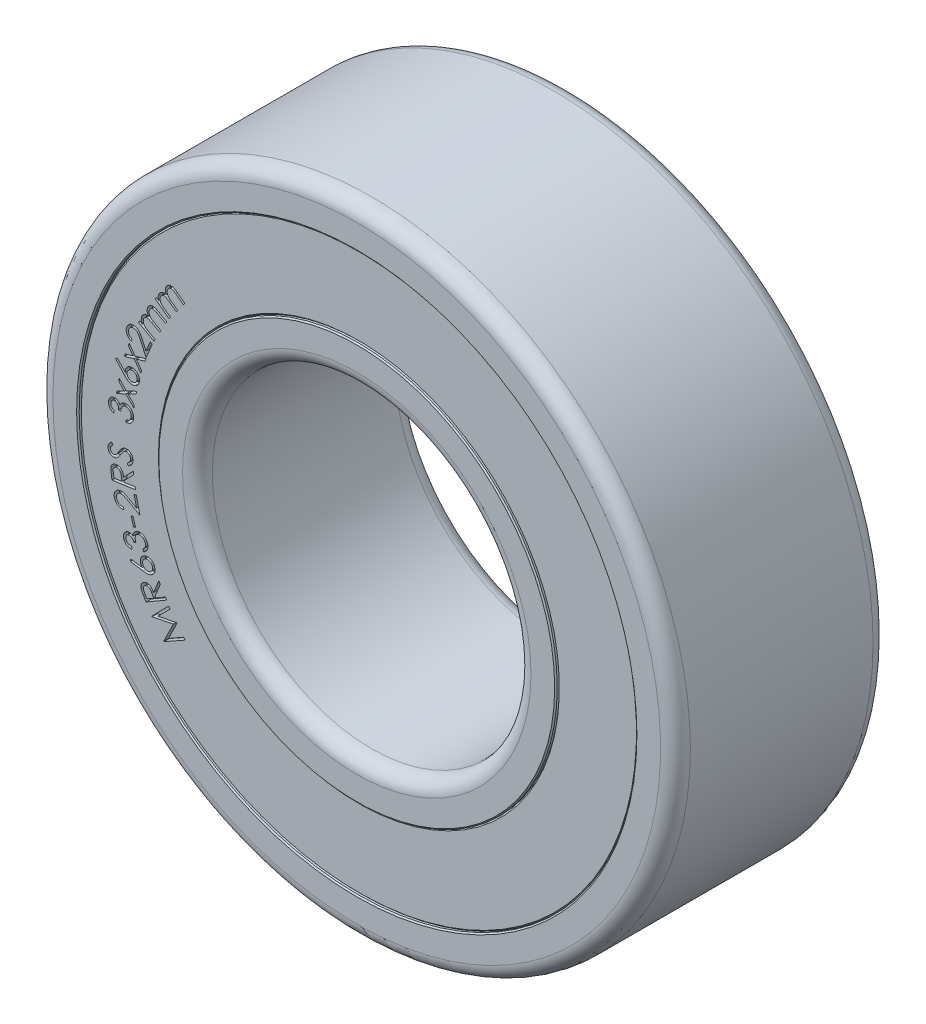
from build123d import *

# Parameters (mm, degrees)
SKETCH_R_INNER_BODY_W          = 2
SKETCH_R_INNER_BODY_H          = 0.375
FILLET_INNER_BODY_R            = 0.14
CHAMFER_INNER_BODY_SIZE        = 0.012
SKETCH_R_OUTER_BODY_W          = 2
SKETCH_R_OUTER_BODY_H          = 0.375
FILLET_OUTER_BODY_R            = 0.14
CHAMFER_OUTER_BODY_SIZE        = 0.012
SKETCH_R_SEAL_FACES_W          = 1.96
SKETCH_R_SEAL_FACES_H          = 0.75
CHAMFER_SEALS_SIZE             = 0.012
CUT_EXTRUDE_SEAL_LABEL_1_DEPTH = 0.05
CUT_EXTRUDE_SEAL_LABEL_2_DEPTH = 0.05


with BuildPart() as part:
    # Sketch R, INNER BODY → Revolve INNER BODY (revolve)
    with BuildSketch(Plane(origin=(0, 0, 0), x_dir=(0, 0, -1), z_dir=(1, 0, 0)), mode=Mode.PRIVATE) as revolve_inner_body_sk:
        with Locations((0, 1.6875)):
            Rectangle(SKETCH_R_INNER_BODY_W, SKETCH_R_INNER_BODY_H)
    revolve(revolve_inner_body_sk.sketch.rotate(Axis((0, 0, 17.5), (0, 0, -1)), 90), axis=Axis((0, 0, 17.5), (0, 0, -1)))

    # Fillet INNER BODY
    fillet_inner_body_edges = [part.edges().sort_by_distance(p)[0] for p in [
        (-1.5, 0, -1),
        (-1.5, 0, 1),
    ]]
    fillet(fillet_inner_body_edges, radius=FILLET_INNER_BODY_R)

    # Chamfer INNER BODY
    chamfer_inner_body_edges = [part.edges().sort_by_distance(p)[0] for p in [
        (-1.875, 0, 1),
        (-1.875, 0, -1),
    ]]
    chamfer(chamfer_inner_body_edges, length=CHAMFER_INNER_BODY_SIZE)


with BuildPart() as body_2:
    # Sketch R, OUTER BODY → Revolve OUTER BODY (revolve)
    with BuildSketch(Plane(origin=(0, 0, 0), x_dir=(0, 0, -1), z_dir=(1, 0, 0)), mode=Mode.PRIVATE) as revolve_outer_body_sk:
        with Locations((0, 2.8125)):
            Rectangle(SKETCH_R_OUTER_BODY_W, SKETCH_R_OUTER_BODY_H)
    revolve(revolve_outer_body_sk.sketch.rotate(Axis((0, 0, 17.5), (0, 0, -1)), 90), axis=Axis((0, 0, 17.5), (0, 0, -1)))

    # Fillet OUTER BODY
    fillet_outer_body_edges = [body_2.edges().sort_by_distance(p)[0] for p in [
        (-3, 0, 1),
        (-3, 0, -1),
    ]]
    fillet(fillet_outer_body_edges, radius=FILLET_OUTER_BODY_R)

    # Chamfer OUTER BODY
    chamfer_outer_body_edges = [body_2.edges().sort_by_distance(p)[0] for p in [
        (-2.625, 0, -1),
        (-2.625, 0, 1),
    ]]
    chamfer(chamfer_outer_body_edges, length=CHAMFER_OUTER_BODY_SIZE)


with BuildPart() as body_3:
    # Sketch R, SEAL FACES → Revolve SEALS (revolve)
    with BuildSketch(Plane(origin=(0, 0, 0), x_dir=(0, 0, -1), z_dir=(1, 0, 0)), mode=Mode.PRIVATE) as revolve_seals_sk:
        with Locations((0, 2.25)):
            Rectangle(SKETCH_R_SEAL_FACES_W, SKETCH_R_SEAL_FACES_H)
    revolve(revolve_seals_sk.sketch.rotate(Axis((0, 0, 17.5), (0, 0, -1)), 270), axis=Axis((0, 0, 17.5), (0, 0, -1)))

    # Chamfer SEALS
    chamfer_seals_edges = [body_3.edges().sort_by_distance(p)[0] for p in [
        (1.875, 0, -0.98),
        (1.875, 0, 0.98),
        (2.625, 0, 0.98),
        (2.625, 0, -0.98),
    ]]
    chamfer(chamfer_seals_edges, length=CHAMFER_SEALS_SIZE)

    # Sketch TEXT RADIUS 1 — MANUALLY ASSIGN TEXT AND FONT SIZE (FROM EQUATIONS) → Cut-Extrude SEAL LABEL 1 (cut)
    # profile 1 of 15: a face of its own
    with BuildSketch(Plane.XY.offset(0.98)):
        with BuildLine():
            Line((-1.91911258, 1.270431739), (-1.90653746, 1.287468998))
            Line((-1.90653746, 1.287468998), (-1.883505609, 1.270476811))
            add(Edge.make_bspline(
                [(-1.883505609, 1.270476811), (-1.884429183, 1.273437831), (-1.8861938, 1.279095269), (-1.887910407, 1.287451138), (-1.888827932, 1.295217532), (-1.888642311, 1.300192746), (-1.888553686, 1.302568157)],
                knots=[0, 0, 0, 0, 1.138074644, 2.174448567, 3.128392412, 4, 4, 4, 4], degree=3))
            add(Edge.make_bspline(
                [(-1.888553686, 1.302568157), (-1.888174733, 1.305620155), (-1.88742848, 1.311630304), (-1.884819203, 1.32026467), (-1.881208999, 1.3283903), (-1.877902368, 1.333260822), (-1.876248999, 1.335696162)],
                knots=[0, 0, 0, 0, 1.030084308, 2.028494238, 3.014214903, 4, 4, 4, 4], degree=3))
            add(Edge.make_bspline(
                [(-1.876248999, 1.335696162), (-1.87503431, 1.337256494), (-1.872617821, 1.340360604), (-1.868440364, 1.344497804), (-1.863898736, 1.348187844), (-1.859009322, 1.351355532), (-1.853932924, 1.354013691), (-1.848748927, 1.355991981), (-1.843582203, 1.35744436), (-1.838276929, 1.358165316), (-1.832680396, 1.358243453), (-1.826635948, 1.357634329), (-1.820060264, 1.35627782), (-1.815558606, 1.354988465), (-1.813193109, 1.354310945)],
                knots=[0, 0, 0, 0, 1.003547845, 1.996448362, 2.978526833, 3.971251372, 4.950836048, 5.883364095, 6.784933055, 7.670994759, 8.594517512, 9.621923091, 10.750386766, 12, 12, 12, 12], degree=3))
            add(Edge.make_bspline(
                [(-1.813193109, 1.354310945), (-1.81461492, 1.35761557), (-1.817379282, 1.364040605), (-1.820021829, 1.373961457), (-1.821446916, 1.383693678), (-1.821426922, 1.393236079), (-1.820188179, 1.402462653), (-1.817676929, 1.411222588), (-1.814042032, 1.419529521), (-1.810660328, 1.424505125), (-1.80895633, 1.427012268)],
                knots=[0, 0, 0, 0, 1.126586004, 2.190370687, 3.208228692, 4.202099219, 5.172006646, 6.117285058, 7.051324372, 8, 8, 8, 8], degree=3))
            add(Edge.make_bspline(
                [(-1.80895633, 1.427012268), (-1.807214663, 1.429201434), (-1.803814333, 1.433475435), (-1.797755708, 1.438848648), (-1.791158085, 1.443192392), (-1.784023967, 1.44643575), (-1.77651726, 1.448569517), (-1.768749712, 1.449521551), (-1.760800172, 1.449296083), (-1.754075194, 1.448043246), (-1.748517443, 1.446462599), (-1.744017083, 1.444761448), (-1.739278068, 1.442589078), (-1.734242891, 1.439996643), (-1.728936769, 1.436971965), (-1.723339713, 1.433512197), (-1.717538478, 1.429505043), (-1.713594122, 1.426673079), (-1.711555489, 1.425209383)],
                knots=[0, 0, 0, 0, 1.209598063, 2.361549057, 3.489399002, 4.61908654, 5.74157537, 6.856040644, 7.995094671, 9.171768459, 9.808082596, 10.49571395, 11.252788099, 12.064633605, 12.94749263, 13.897156365, 14.913148778, 16, 16, 16, 16], degree=3))
            Line((-1.711555489, 1.425209383), (-1.638764023, 1.371528493))
            Line((-1.638764023, 1.371528493), (-1.65169972, 1.353995441))
            Line((-1.65169972, 1.353995441), (-1.724491186, 1.40767633))
            add(Edge.make_bspline(
                [(-1.724491186, 1.40767633), (-1.726216921, 1.408926006), (-1.729532638, 1.411327054), (-1.734331953, 1.414736354), (-1.738847285, 1.417650675), (-1.742985421, 1.420194291), (-1.746787174, 1.422303989), (-1.750195571, 1.424108143), (-1.753308579, 1.425416293), (-1.75695003, 1.426626983), (-1.761315702, 1.427450856), (-1.76653393, 1.427658523), (-1.77176327, 1.426945182), (-1.776945928, 1.425458978), (-1.781969428, 1.423168277), (-1.786655421, 1.419986626), (-1.791040909, 1.416048295), (-1.793526294, 1.412900133), (-1.794803686, 1.411282099)],
                knots=[0, 0, 0, 0, 1.261595965, 2.423950748, 3.48490634, 4.442982565, 5.29921915, 6.059096048, 6.724894255, 7.29594194, 8.32874143, 9.343454129, 10.375103721, 11.43937312, 12.526010364, 13.628838918, 14.781314523, 16, 16, 16, 16], degree=3))
            add(Edge.make_bspline(
                [(-1.794803686, 1.411282099), (-1.796232674, 1.409176726), (-1.799067564, 1.404999992), (-1.801950905, 1.397992638), (-1.80387009, 1.39064127), (-1.804493562, 1.382966795), (-1.80404908, 1.375245428), (-1.802517144, 1.36763642), (-1.799755751, 1.360308539), (-1.796583698, 1.354378413), (-1.79330198, 1.349646239), (-1.790112681, 1.34589643), (-1.786348968, 1.341869694), (-1.781991022, 1.33760987), (-1.776986957, 1.333128483), (-1.771379463, 1.328424447), (-1.7651251, 1.323501476), (-1.7607211, 1.320197223), (-1.758430489, 1.318478614)],
                knots=[0, 0, 0, 0, 1.07902924, 2.140626135, 3.201608191, 4.297829792, 5.39809904, 6.480204244, 7.583434792, 8.714915767, 9.329645064, 10.027926854, 10.805095538, 11.67215235, 12.617234881, 13.659759621, 14.782792878, 16, 16, 16, 16], degree=3))
            Line((-1.758430489, 1.318478614), (-1.706236979, 1.279987027))
            Line((-1.706236979, 1.279987027), (-1.7188121, 1.262949768))
            Line((-1.7188121, 1.262949768), (-1.787051282, 1.313250248))
            add(Edge.make_bspline(
                [(-1.787051282, 1.313250248), (-1.788982922, 1.314671406), (-1.792697155, 1.317404063), (-1.798121841, 1.321178177), (-1.803152051, 1.324458604), (-1.807697919, 1.327390776), (-1.811878687, 1.329797906), (-1.815609336, 1.331827402), (-1.81896746, 1.333314971), (-1.822814747, 1.334767741), (-1.827401833, 1.335834141), (-1.832863867, 1.336197412), (-1.838317589, 1.335707869), (-1.843694811, 1.334280734), (-1.848877477, 1.332060388), (-1.853667874, 1.328895097), (-1.858163902, 1.325032098), (-1.860644882, 1.321861137), (-1.861916066, 1.320236426)],
                knots=[0, 0, 0, 0, 1.333613441, 2.564323257, 3.674336538, 4.673365961, 5.571887803, 6.356785721, 7.033761586, 7.612685744, 8.642239241, 9.638749921, 10.645575135, 11.673024521, 12.720758786, 13.765958099, 14.855340314, 16, 16, 16, 16], degree=3))
            add(Edge.make_bspline(
                [(-1.861916066, 1.320236426), (-1.863278098, 1.318218071), (-1.865994542, 1.314192656), (-1.868825262, 1.30741958), (-1.870573864, 1.300208036), (-1.871336005, 1.292668782), (-1.871035166, 1.285000309), (-1.869584219, 1.277428295), (-1.866943807, 1.270106391), (-1.863917439, 1.264158379), (-1.860752511, 1.259475846), (-1.857852578, 1.255765713), (-1.854408362, 1.251952857), (-1.850480014, 1.247985533), (-1.846032507, 1.243879011), (-1.841095615, 1.239595183), (-1.835566772, 1.235243076), (-1.831693148, 1.232323506), (-1.829689503, 1.230813349)],
                knots=[0, 0, 0, 0, 1.08710415, 2.168125268, 3.2618569, 4.396690645, 5.546882982, 6.683049263, 7.830883035, 9.018175381, 9.657520088, 10.356596123, 11.122896718, 11.954547357, 12.853331199, 13.830139053, 14.877632607, 16, 16, 16, 16], degree=3))
            Line((-1.829689503, 1.230813349), (-1.773214143, 1.189166715))
            Line((-1.773214143, 1.189166715), (-1.785789263, 1.172129455))
            Line((-1.785789263, 1.172129455), (-1.91911258, 1.270431739))
        make_face()
    # profile 2 of 15: a face of its own
    with BuildSketch(Plane.XY.offset(0.98)):
        with BuildLine():
            Line((-2.073939331, 0.998426037), (-2.063753033, 1.01704082))
            Line((-2.063753033, 1.01704082), (-2.038602792, 1.003293825))
            add(Edge.make_bspline(
                [(-2.038602792, 1.003293825), (-2.03991314, 1.006098231), (-2.042425066, 1.011474253), (-2.045266359, 1.019510592), (-2.047229092, 1.027098604), (-2.047734687, 1.032055317), (-2.047977792, 1.034438657)],
                knots=[0, 0, 0, 0, 1.134578598, 2.174977053, 3.122472913, 4, 4, 4, 4], degree=3))
            add(Edge.make_bspline(
                [(-2.047977792, 1.034438657), (-2.048010245, 1.037524808), (-2.048074105, 1.043597731), (-2.046573604, 1.052501516), (-2.044121857, 1.061052483), (-2.041495896, 1.06632328), (-2.040180316, 1.068963897)],
                knots=[0, 0, 0, 0, 1.03208424, 2.030933473, 3.013517298, 4, 4, 4, 4], degree=3))
            add(Edge.make_bspline(
                [(-2.040180316, 1.068963897), (-2.039182319, 1.070687178), (-2.037205872, 1.074099985), (-2.03358057, 1.078740224), (-2.029607401, 1.083040432), (-2.025152914, 1.086809424), (-2.02048235, 1.090164262), (-2.015578159, 1.092798344), (-2.010640911, 1.094944882), (-2.005465048, 1.09635256), (-1.999930017, 1.097170685), (-1.993841442, 1.09736798), (-1.987131162, 1.096942216), (-1.982483545, 1.096239354), (-1.980054114, 1.09587195)],
                knots=[0, 0, 0, 0, 1.008326425, 1.996902608, 2.977526463, 3.971252125, 4.949536963, 5.886764045, 6.787770022, 7.672798988, 8.596907765, 9.618122591, 10.754930995, 12, 12, 12, 12], degree=3))
            add(Edge.make_bspline(
                [(-1.980054114, 1.09587195), (-1.981901007, 1.098957334), (-1.985502276, 1.104973544), (-1.989541029, 1.114450242), (-1.992190518, 1.123970604), (-1.993526878, 1.133446134), (-1.993481584, 1.14278206), (-1.992152269, 1.151812966), (-1.989675036, 1.160553049), (-1.986992226, 1.165949548), (-1.985643057, 1.168663416)],
                knots=[0, 0, 0, 0, 1.123584182, 2.190883985, 3.209967787, 4.206002623, 5.173891502, 6.118755876, 7.053933173, 8, 8, 8, 8], degree=3))
            add(Edge.make_bspline(
                [(-1.985643057, 1.168663416), (-1.984208149, 1.171068737), (-1.981406177, 1.175765654), (-1.976124545, 1.181919707), (-1.970167375, 1.187128841), (-1.963514696, 1.191321035), (-1.956353233, 1.194492624), (-1.948763107, 1.196506587), (-1.940828086, 1.197300107), (-1.933983778, 1.196999336), (-1.928249625, 1.196094761), (-1.92356847, 1.195001041), (-1.918548905, 1.193491023), (-1.913194118, 1.191596293), (-1.907515651, 1.189282111), (-1.901507314, 1.186580244), (-1.895208315, 1.183394336), (-1.890912362, 1.181111059), (-1.888692936, 1.179931445)],
                knots=[0, 0, 0, 0, 1.208125775, 2.359130542, 3.48622643, 4.615208142, 5.742752432, 6.857352102, 7.99269621, 9.175076927, 9.805708625, 10.498443074, 11.250033409, 12.06907606, 12.951307492, 13.898295389, 14.914192768, 16, 16, 16, 16], degree=3))
            Line((-1.888692936, 1.179931445), (-1.809230797, 1.136436854))
            Line((-1.809230797, 1.136436854), (-1.819687528, 1.117326277))
            Line((-1.819687528, 1.117326277), (-1.899149667, 1.160820868))
            add(Edge.make_bspline(
                [(-1.899149667, 1.160820868), (-1.901041976, 1.161828569), (-1.904666048, 1.163758477), (-1.909885251, 1.166514524), (-1.914771334, 1.168778113), (-1.919205076, 1.170803377), (-1.923284504, 1.172364318), (-1.92692497, 1.173652972), (-1.930174262, 1.174574992), (-1.933941273, 1.17530117), (-1.938387655, 1.175569596), (-1.943591329, 1.175014985), (-1.948693108, 1.173631588), (-1.953654607, 1.171485567), (-1.958300305, 1.168473543), (-1.962600665, 1.16475549), (-1.96636213, 1.160187619), (-1.968410663, 1.156734148), (-1.969462167, 1.154961493)],
                knots=[0, 0, 0, 0, 1.2663174, 2.425198716, 3.48502883, 4.44637305, 5.303262483, 6.063757316, 6.726848222, 7.295936607, 8.327147903, 9.344328459, 10.373208208, 11.438189364, 12.52371161, 13.630603393, 14.78379729, 16, 16, 16, 16], degree=3))
            add(Edge.make_bspline(
                [(-1.969462167, 1.154961493), (-1.970594115, 1.15267981), (-1.972836446, 1.148159914), (-1.974780748, 1.140821495), (-1.975661735, 1.133260133), (-1.975334021, 1.125534635), (-1.973844309, 1.117918208), (-1.971291663, 1.110570845), (-1.967604079, 1.103650094), (-1.963617279, 1.098205219), (-1.959687797, 1.093986234), (-1.956040513, 1.090666416), (-1.951817737, 1.087131722), (-1.946859744, 1.083565384), (-1.941324106, 1.079753986), (-1.935081257, 1.075870953), (-1.928258339, 1.071747362), (-1.923423318, 1.069082091), (-1.920919499, 1.067701878)],
                knots=[0, 0, 0, 0, 1.078185085, 2.135828531, 3.200763846, 4.297940774, 5.401688567, 6.482131949, 7.585530038, 8.716275429, 9.334126024, 10.028708706, 10.807234968, 11.668999926, 12.618332915, 13.6580993, 14.787244838, 16, 16, 16, 16], degree=3))
            Line((-1.920919499, 1.067701878), (-1.863903273, 1.036511974))
            Line((-1.863903273, 1.036511974), (-1.874089571, 1.01789719))
            Line((-1.874089571, 1.01789719), (-1.94863885, 1.058687455))
            add(Edge.make_bspline(
                [(-1.94863885, 1.058687455), (-1.950753391, 1.059836349), (-1.954798602, 1.062034236), (-1.960663928, 1.065076757), (-1.966078304, 1.067664685), (-1.97097119, 1.069974831), (-1.975469639, 1.07174153), (-1.979436198, 1.073280129), (-1.98297225, 1.074308527), (-1.986976757, 1.075244673), (-1.991680085, 1.075633999), (-1.997167263, 1.075280055), (-2.002535894, 1.074062221), (-2.007683277, 1.071916221), (-2.01250396, 1.06898717), (-2.016904583, 1.065296657), (-2.020730186, 1.060755798), (-2.022799523, 1.057306892), (-2.02386421, 1.055532407)],
                knots=[0, 0, 0, 0, 1.336451548, 2.55669229, 3.668732942, 4.66929683, 5.56018205, 6.352159246, 7.030658762, 7.60351424, 8.633865255, 9.637312368, 10.647294187, 11.676123889, 12.720700271, 13.768703194, 14.851982445, 16, 16, 16, 16], degree=3))
            add(Edge.make_bspline(
                [(-2.02386421, 1.055532407), (-2.024949137, 1.053339682), (-2.027100059, 1.048992493), (-2.028952917, 1.041881574), (-2.02983692, 1.034507775), (-2.029527476, 1.026899484), (-2.028204515, 1.01932065), (-2.025755222, 1.011988992), (-2.022158055, 1.005060903), (-2.018333641, 0.999583327), (-2.014562451, 0.995352911), (-2.011175646, 0.992067476), (-2.007243829, 0.988747705), (-2.00278435, 0.985365147), (-1.997844927, 0.981845534), (-1.992333448, 0.978294187), (-1.986288002, 0.97470198), (-1.982057844, 0.972334604), (-1.979873826, 0.971112335)],
                knots=[0, 0, 0, 0, 1.089910874, 2.160804464, 3.261747334, 4.396253458, 5.547770445, 6.687027287, 7.833196597, 9.022552654, 9.659361375, 10.361516346, 11.127763101, 11.955671523, 12.860343875, 13.835434466, 14.882441476, 16, 16, 16, 16], degree=3))
            Line((-1.979873826, 0.971112335), (-1.9181701, 0.93735332))
            Line((-1.9181701, 0.93735332), (-1.928356398, 0.918738537))
            Line((-1.928356398, 0.918738537), (-2.073939331, 0.998426037))
        make_face()
    # profile 3 of 15: a face of its own
    with BuildSketch(Plane.XY.offset(0.98)):
        with BuildLine():
            Line((-2.134442911, 0.83041783), (-2.142691108, 0.810541027))
            add(Edge.make_bspline(
                [(-2.142691108, 0.810541027), (-2.145147489, 0.811699916), (-2.149970458, 0.813975329), (-2.156704623, 0.818068051), (-2.162870653, 0.822579044), (-2.168443668, 0.827558451), (-2.173418553, 0.832973329), (-2.177789262, 0.838854769), (-2.181566916, 0.845170616), (-2.184768106, 0.851865644), (-2.187257763, 0.858803627), (-2.189110576, 0.865841209), (-2.190130278, 0.872933016), (-2.190451362, 0.880043587), (-2.190054796, 0.887176979), (-2.188845096, 0.894325291), (-2.186969379, 0.901533109), (-2.185165165, 0.906229511), (-2.184247599, 0.90861795)],
                knots=[0, 0, 0, 0, 1.097830309, 2.155529112, 3.181241222, 4.183891268, 5.173028318, 6.15009139, 7.142135589, 8.145024956, 9.146422241, 10.119092125, 11.083241106, 12.038155468, 12.993688248, 13.966642774, 14.965899373, 16, 16, 16, 16], degree=3))
            add(Edge.make_bspline(
                [(-2.184247599, 0.90861795), (-2.183217984, 0.910919507), (-2.181198766, 0.91543318), (-2.177599857, 0.921767334), (-2.173498177, 0.927472144), (-2.169055649, 0.932660385), (-2.164079055, 0.937189675), (-2.15870231, 0.941187355), (-2.152856828, 0.944566687), (-2.146660834, 0.947353322), (-2.140255119, 0.949462714), (-2.133832905, 0.951097318), (-2.127409099, 0.951983306), (-2.121009529, 0.952265151), (-2.114637675, 0.951899774), (-2.108278479, 0.950905232), (-2.101957558, 0.949232953), (-2.097846853, 0.947672282), (-2.095771036, 0.946884176)],
                knots=[0, 0, 0, 0, 1.123881943, 2.204088332, 3.241398016, 4.252881782, 5.243836136, 6.235333802, 7.234968148, 8.248468701, 9.258975874, 10.238725954, 11.199395149, 12.144830918, 13.090931016, 14.040322155, 15.010405229, 16, 16, 16, 16], degree=3))
            add(Edge.make_bspline(
                [(-2.095771036, 0.946884176), (-2.092903072, 0.945597549), (-2.087220731, 0.943048333), (-2.079488607, 0.937817586), (-2.072375447, 0.931818442), (-2.067093455, 0.925927085), (-2.063014719, 0.920616529), (-2.05990028, 0.915888373), (-2.056547057, 0.910596133), (-2.053149974, 0.904608536), (-2.049538297, 0.898038346), (-2.045785768, 0.890822118), (-2.041983855, 0.882918678), (-2.039410954, 0.877430324), (-2.038078729, 0.874588503)],
                knots=[0, 0, 0, 0, 1.190058907, 2.357882056, 3.525913677, 4.711750444, 5.349919985, 6.064205346, 6.857805245, 7.725655373, 8.674218012, 9.701214389, 10.809709242, 12, 12, 12, 12], degree=3))
            Line((-2.038078729, 0.874588503), (-2.003823921, 0.800039224))
            Line((-2.003823921, 0.800039224), (-1.964160459, 0.895682253))
            Line((-1.964160459, 0.895682253), (-1.94414844, 0.887388984))
            Line((-1.94414844, 0.887388984), (-2.002471757, 0.74667384))
            Line((-2.002471757, 0.74667384), (-2.05516106, 0.861247157))
            add(Edge.make_bspline(
                [(-2.05516106, 0.861247157), (-2.05644731, 0.864029352), (-2.058920815, 0.869379618), (-2.062569851, 0.87702803), (-2.065966701, 0.88400044), (-2.069278987, 0.890210517), (-2.072336663, 0.895759481), (-2.075153618, 0.900637194), (-2.077798488, 0.904801056), (-2.081088424, 0.909345069), (-2.085270391, 0.914273282), (-2.090866871, 0.919269089), (-2.096997866, 0.923455599), (-2.101462426, 0.925520187), (-2.103703729, 0.926556652)],
                knots=[0, 0, 0, 0, 1.322616911, 2.543441605, 3.656787029, 4.668907736, 5.580067111, 6.39065289, 7.099203527, 7.707399901, 8.81069602, 9.880474019, 10.935953787, 12, 12, 12, 12], degree=3))
            add(Edge.make_bspline(
                [(-2.103703729, 0.926556652), (-2.105151272, 0.927111865), (-2.108018527, 0.928211614), (-2.112446446, 0.929331104), (-2.116888036, 0.929976586), (-2.121332225, 0.930101348), (-2.125784769, 0.929777981), (-2.130261626, 0.929023007), (-2.134746994, 0.927723242), (-2.139202616, 0.926038981), (-2.143513783, 0.92394197), (-2.147534047, 0.921431222), (-2.151302766, 0.91866078), (-2.154699557, 0.91546684), (-2.157783505, 0.911935828), (-2.160521297, 0.908041213), (-2.162994667, 0.90383107), (-2.164324942, 0.900820064), (-2.165001805, 0.899288023)],
                knots=[0, 0, 0, 0, 0.996690352, 1.974216797, 2.931025163, 3.878660828, 4.828266017, 5.799128031, 6.793519426, 7.827472552, 8.860567007, 9.87177303, 10.873092108, 11.864661194, 12.864813424, 13.883887441, 14.923292305, 16, 16, 16, 16], degree=3))
            add(Edge.make_bspline(
                [(-2.165001805, 0.899288023), (-2.165633217, 0.897645613), (-2.166867875, 0.894434057), (-2.168176796, 0.889512583), (-2.169017, 0.884640013), (-2.1692608, 0.879773196), (-2.169099552, 0.874957874), (-2.16842465, 0.870161878), (-2.167170261, 0.865437786), (-2.165536545, 0.860731525), (-2.163310366, 0.856199211), (-2.160629061, 0.85183486), (-2.157482102, 0.847674944), (-2.153775831, 0.843803338), (-2.149673999, 0.840076901), (-2.14503163, 0.836620658), (-2.139964899, 0.833309344), (-2.136308146, 0.831394535), (-2.134442911, 0.83041783)],
                knots=[0, 0, 0, 0, 1.006291302, 1.967693882, 2.909012833, 3.830371944, 4.750928478, 5.66281269, 6.59489932, 7.543921149, 8.509045276, 9.477800361, 10.471675137, 11.487361156, 12.540489824, 13.63923357, 14.79582169, 16, 16, 16, 16], degree=3))
        make_face()
    # profile 4 of 15: a face of its own
    with BuildSketch(Plane.XY.offset(0.98)):
        Polygon((-2.207528582, 0.654493006), (-2.199145169, 0.67865166), (-2.126894568, 0.69997077), (-2.170479303, 0.761404064), (-2.162140962, 0.785517645), (-2.106386755, 0.706325939), (-2.003487116, 0.738146852), (-2.011915601, 0.713717766), (-2.094172212, 0.688657669), (-2.044818246, 0.618750819), (-2.053156587, 0.594772453), (-2.114680025, 0.682347573), align=None)
    # profile 5 of 15: a face of its own
    with BuildSketch(Plane.XY.offset(0.98)):
        with BuildLine():
            Line((-2.289758317, 0.594109126), (-2.273667572, 0.60911814))
            Line((-2.273667572, 0.60911814), (-2.199163365, 0.528393982))
            add(Edge.make_bspline(
                [(-2.199163365, 0.528393982), (-2.199306884, 0.530481615), (-2.199586585, 0.534550149), (-2.19935643, 0.540515593), (-2.198834836, 0.546179086), (-2.198056515, 0.549793784), (-2.197675985, 0.551561049)],
                knots=[0, 0, 0, 0, 1.076524121, 2.098009595, 3.070096342, 4, 4, 4, 4], degree=3))
            add(Edge.make_bspline(
                [(-2.197675985, 0.551561049), (-2.197102204, 0.553662975), (-2.195968917, 0.557814535), (-2.193555846, 0.563735287), (-2.190615566, 0.569256366), (-2.187165148, 0.574399072), (-2.18318472, 0.579135798), (-2.178695761, 0.583499773), (-2.173646334, 0.587430267), (-2.168147709, 0.590944752), (-2.162348874, 0.594018991), (-2.156303649, 0.596392895), (-2.150162327, 0.598245012), (-2.143852122, 0.599334648), (-2.13744031, 0.599918747), (-2.130892413, 0.599724146), (-2.124210519, 0.599063087), (-2.119783063, 0.598048921), (-2.117537764, 0.597534607)],
                knots=[0, 0, 0, 0, 1.015111772, 2.004969025, 2.973252494, 3.927139551, 4.886770188, 5.852719951, 6.840592526, 7.864559144, 8.892208676, 9.895066303, 10.88804138, 11.877303648, 12.875502611, 13.88438434, 14.927106048, 16, 16, 16, 16], degree=3))
            add(Edge.make_bspline(
                [(-2.117537764, 0.597534607), (-2.114503941, 0.596685567), (-2.108520285, 0.595010992), (-2.100159962, 0.591105919), (-2.092485925, 0.586304852), (-2.085644856, 0.580509869), (-2.079600863, 0.573919959), (-2.074575605, 0.566520535), (-2.070564429, 0.55838828), (-2.067645984, 0.549649199), (-2.065728241, 0.540557955), (-2.065071614, 0.531316787), (-2.065515954, 0.522034452), (-2.0667796, 0.515957316), (-2.067417572, 0.512889174)],
                knots=[0, 0, 0, 0, 1.032773734, 2.036955583, 3.016735741, 3.996863453, 4.970978475, 5.943656426, 6.923039228, 7.938435815, 8.960899605, 9.964887624, 10.972539956, 12, 12, 12, 12], degree=3))
            add(Edge.make_bspline(
                [(-2.067417572, 0.512889174), (-2.068244036, 0.509978608), (-2.069879429, 0.504219236), (-2.073631846, 0.496084654), (-2.078433258, 0.488584916), (-2.084115762, 0.48171407), (-2.090666165, 0.475648707), (-2.097953524, 0.47056311), (-2.105964664, 0.466562043), (-2.11451335, 0.463619309), (-2.123392042, 0.461775033), (-2.132387537, 0.461092294), (-2.141399009, 0.46154987), (-2.147296883, 0.462781294), (-2.15026012, 0.463399991)],
                knots=[0, 0, 0, 0, 1.012403567, 2.003324846, 2.987641833, 3.988394161, 4.98207233, 5.969151822, 6.95499878, 7.972057846, 8.989714465, 9.984067925, 10.987146176, 12, 12, 12, 12], degree=3))
            add(Edge.make_bspline(
                [(-2.15026012, 0.463399991), (-2.152501124, 0.464009794), (-2.157052101, 0.465248166), (-2.163699765, 0.468119548), (-2.170420375, 0.471505977), (-2.175968113, 0.474974169), (-2.180446003, 0.478164084), (-2.183991368, 0.480885403), (-2.187626919, 0.483942277), (-2.191354424, 0.487358111), (-2.195289645, 0.490978742), (-2.199307946, 0.494972269), (-2.203431092, 0.499279412), (-2.206185525, 0.5022917), (-2.207591851, 0.503829679)],
                knots=[0, 0, 0, 0, 1.172636158, 2.381361843, 3.651674798, 4.975157444, 5.683217369, 6.430590614, 7.233798844, 8.083386573, 8.986165134, 9.936715986, 10.946553002, 12, 12, 12, 12], degree=3))
            Line((-2.207591851, 0.503829679), (-2.289758317, 0.594109126))
        make_face()
        with BuildLine():
            add(Edge.make_bspline(
                [(-2.1798725, 0.541690256), (-2.180217674, 0.54013313), (-2.180899845, 0.537055764), (-2.181395505, 0.532402801), (-2.181388822, 0.527811905), (-2.180941463, 0.523296594), (-2.180036435, 0.518855793), (-2.178664103, 0.514497144), (-2.176854552, 0.5101881), (-2.174579761, 0.506012251), (-2.17193047, 0.502066501), (-2.168995681, 0.498423242), (-2.165731972, 0.495178613), (-2.162216512, 0.492271324), (-2.158395123, 0.489784095), (-2.15431737, 0.487665951), (-2.149970029, 0.485863996), (-2.14690591, 0.485045373), (-2.145347259, 0.484628958)],
                knots=[0, 0, 0, 0, 1.031097684, 2.037770496, 3.019314675, 3.995987638, 4.968007904, 5.945454163, 6.947189393, 7.986498036, 9.016129139, 10.017864368, 11.007410334, 11.987943679, 12.963697557, 13.950423957, 14.95742508, 16, 16, 16, 16], degree=3))
            add(Edge.make_bspline(
                [(-2.145347259, 0.484628958), (-2.143790141, 0.484283816), (-2.140712788, 0.483601708), (-2.136059725, 0.483105586), (-2.131469199, 0.483113969), (-2.126967194, 0.483553614), (-2.122531482, 0.484479543), (-2.118167251, 0.485829016), (-2.113852486, 0.487634099), (-2.109701192, 0.489949284), (-2.105727493, 0.492554294), (-2.102082213, 0.495508502), (-2.098848337, 0.498752211), (-2.095961413, 0.502257908), (-2.093499629, 0.506053156), (-2.091355056, 0.510102338), (-2.089576156, 0.51442967), (-2.088749618, 0.517476147), (-2.088331033, 0.519018982)],
                knots=[0, 0, 0, 0, 1.03318296, 2.041891652, 3.025420891, 4.004069062, 4.968515846, 5.957237787, 6.960998911, 7.993860586, 9.033676405, 10.037437529, 11.028984738, 11.997796999, 12.975524226, 13.955624757, 14.964662424, 16, 16, 16, 16], degree=3))
            add(Edge.make_bspline(
                [(-2.088331033, 0.519018982), (-2.087985898, 0.520576098), (-2.087303802, 0.523653445), (-2.086807592, 0.528306546), (-2.086816299, 0.532896934), (-2.087254753, 0.537399445), (-2.088185096, 0.541833281), (-2.089519378, 0.546210346), (-2.091392802, 0.550502535), (-2.09369307, 0.55466613), (-2.096300167, 0.558640601), (-2.099256908, 0.562267743), (-2.102454214, 0.565532901), (-2.105962204, 0.568402609), (-2.109754634, 0.57086721), (-2.113804579, 0.573011021), (-2.118131703, 0.574790128), (-2.121178209, 0.575616637), (-2.122721057, 0.576035208)],
                knots=[0, 0, 0, 0, 1.033379485, 2.042280046, 3.025996366, 4.004830689, 4.969460923, 5.958370932, 6.966142548, 7.999200687, 9.039214293, 10.043166345, 11.028039185, 11.997035727, 12.974948931, 13.95523589, 14.964465489, 16, 16, 16, 16], degree=3))
            add(Edge.make_bspline(
                [(-2.122721057, 0.576035208), (-2.12429326, 0.576379651), (-2.12738637, 0.5770573), (-2.132068804, 0.57756433), (-2.136671823, 0.577536488), (-2.141206987, 0.577162858), (-2.145666794, 0.576245492), (-2.150028546, 0.574824286), (-2.154359571, 0.573020192), (-2.158533276, 0.570741014), (-2.162482817, 0.568095976), (-2.166105234, 0.565155633), (-2.169373922, 0.561959159), (-2.172230217, 0.55843336), (-2.174766226, 0.554684104), (-2.176834753, 0.550591386), (-2.178631655, 0.546281934), (-2.179455353, 0.543233886), (-2.1798725, 0.541690256)],
                knots=[0, 0, 0, 0, 1.041085892, 2.048204113, 3.039905143, 4.016090749, 4.988541093, 5.97862037, 6.980798825, 8.020567317, 9.050653987, 10.052832442, 11.03596539, 12.003250087, 12.984795279, 13.958848203, 14.966294881, 16, 16, 16, 16], degree=3))
        make_face(mode=Mode.SUBTRACT)
    # profile 6 of 15: a face of its own
    with BuildSketch(Plane.XY.offset(0.98)):
        Polygon((-2.28064482, 0.314768051), (-2.276002392, 0.339873219), (-2.207943497, 0.371829349), (-2.260227151, 0.425870815), (-2.255629796, 0.450930911), (-2.18860756, 0.381204349), (-2.0918828, 0.428124421), (-2.0965703, 0.40274882), (-2.17391405, 0.365564325), (-2.114689291, 0.304040887), (-2.119241574, 0.279116008), (-2.193204916, 0.356279469), align=None)
    # profile 7 of 15: a face of its own
    with BuildSketch(Plane.XY.offset(0.98)):
        with BuildLine():
            Line((-2.302935704, 0.164845302), (-2.305009021, 0.141993739))
            add(Edge.make_bspline(
                [(-2.305009021, 0.141993739), (-2.307200974, 0.142740374), (-2.311508111, 0.144207495), (-2.31762211, 0.146958891), (-2.323388345, 0.149891486), (-2.328651964, 0.153252957), (-2.333533521, 0.156864649), (-2.337936377, 0.160835802), (-2.341950849, 0.165102948), (-2.345494532, 0.169678505), (-2.348558204, 0.174522781), (-2.351181871, 0.179521216), (-2.353324511, 0.184691994), (-2.354929917, 0.190028266), (-2.356122792, 0.19549627), (-2.356789602, 0.201124113), (-2.356988735, 0.206917473), (-2.356712054, 0.210819904), (-2.356571521, 0.212802032)],
                knots=[0, 0, 0, 0, 1.165356099, 2.28989832, 3.372670078, 4.419975488, 5.430683899, 6.427106666, 7.401223836, 8.377248595, 9.336356361, 10.283817044, 11.216667756, 12.149978491, 13.086258588, 14.031178833, 14.999993844, 16, 16, 16, 16], degree=3))
            add(Edge.make_bspline(
                [(-2.356571521, 0.212802032), (-2.356206231, 0.215669605), (-2.355484053, 0.221338786), (-2.353173061, 0.229575994), (-2.349913621, 0.237412509), (-2.345729718, 0.244779386), (-2.340781602, 0.251500108), (-2.335138677, 0.257389323), (-2.328877594, 0.26236812), (-2.322019043, 0.266279702), (-2.31488909, 0.269335784), (-2.307585766, 0.27126379), (-2.300225212, 0.272250019), (-2.295335445, 0.27201125), (-2.292884622, 0.271891576)],
                knots=[0, 0, 0, 0, 1.079083437, 2.133344131, 3.185389989, 4.243887794, 5.291550108, 6.296145127, 7.283459722, 8.269544395, 9.238246225, 10.173842841, 11.084703396, 12, 12, 12, 12], degree=3))
            add(Edge.make_bspline(
                [(-2.292884622, 0.271891576), (-2.290543777, 0.271595772), (-2.285945744, 0.271014738), (-2.27933245, 0.269040446), (-2.273206654, 0.266163402), (-2.267491779, 0.262481505), (-2.262282425, 0.257881003), (-2.257571911, 0.252378941), (-2.253265653, 0.246070448), (-2.250914198, 0.241393112), (-2.249705536, 0.238988931)],
                knots=[0, 0, 0, 0, 0.991137523, 1.946852949, 2.888255408, 3.829488184, 4.796666625, 5.800116389, 6.869245821, 8, 8, 8, 8], degree=3))
            add(Edge.make_bspline(
                [(-2.249705536, 0.238988931), (-2.248310396, 0.241493053), (-2.245567914, 0.246415506), (-2.240437129, 0.253017689), (-2.23471141, 0.258910958), (-2.230314871, 0.262095659), (-2.228115993, 0.263688451)],
                knots=[0, 0, 0, 0, 1.036555264, 2.03759823, 3.018527657, 4, 4, 4, 4], degree=3))
            add(Edge.make_bspline(
                [(-2.228115993, 0.263688451), (-2.226526126, 0.264724985), (-2.223393013, 0.266767659), (-2.218440839, 0.269279844), (-2.213425829, 0.271367431), (-2.208320333, 0.273009641), (-2.203094608, 0.274135477), (-2.197787076, 0.27479835), (-2.192385964, 0.275063113), (-2.188782307, 0.274812446), (-2.186965151, 0.274686047)],
                knots=[0, 0, 0, 0, 1.047216954, 2.063726225, 3.060411935, 4.044172981, 5.020386101, 6.007080418, 6.995064009, 8, 8, 8, 8], degree=3))
            add(Edge.make_bspline(
                [(-2.186965151, 0.274686047), (-2.18383813, 0.274276803), (-2.177596138, 0.273459891), (-2.168496854, 0.270669782), (-2.159748821, 0.26667113), (-2.152835387, 0.262363099), (-2.147609129, 0.258385705), (-2.143907506, 0.255177808), (-2.140440679, 0.251790136), (-2.137309016, 0.248131413), (-2.134409826, 0.244297784), (-2.131790927, 0.2402529), (-2.129378227, 0.23603102), (-2.126657573, 0.23006812), (-2.123798965, 0.222306419), (-2.121773395, 0.212501503), (-2.120854774, 0.202295573), (-2.121265718, 0.195404282), (-2.121475368, 0.191888571)],
                knots=[0, 0, 0, 0, 1.285162989, 2.565373276, 3.865873836, 5.201411611, 5.879528492, 6.544547461, 7.199198016, 7.855568925, 8.507918619, 9.159230273, 9.820849038, 10.490150136, 11.832173936, 13.186188546, 14.564485501, 16, 16, 16, 16], degree=3))
            add(Edge.make_bspline(
                [(-2.121475368, 0.191888571), (-2.12173776, 0.189539143), (-2.122254058, 0.184916264), (-2.123668531, 0.178192953), (-2.125552862, 0.17181031), (-2.127954645, 0.165775991), (-2.130847821, 0.160096372), (-2.134181912, 0.154722122), (-2.138101548, 0.149754945), (-2.142464621, 0.145113415), (-2.147285969, 0.140855112), (-2.152604613, 0.137106073), (-2.158354803, 0.133804266), (-2.164559503, 0.130967615), (-2.171202892, 0.12856619), (-2.17831313, 0.126699849), (-2.185856606, 0.125237291), (-2.191061398, 0.124664024), (-2.193725968, 0.124370542)],
                knots=[0, 0, 0, 0, 1.043375082, 2.053008585, 3.029019152, 3.97881763, 4.9163505, 5.840360326, 6.766653541, 7.705265465, 8.650116256, 9.601766374, 10.573551719, 11.573901441, 12.61054814, 13.688711554, 14.816745847, 16, 16, 16, 16], degree=3))
            Line((-2.193725968, 0.124370542), (-2.191742795, 0.14627559))
            add(Edge.make_bspline(
                [(-2.191742795, 0.14627559), (-2.189934508, 0.146596291), (-2.186431998, 0.147217462), (-2.18141209, 0.148531451), (-2.176709341, 0.14988222), (-2.172391896, 0.151509447), (-2.168420084, 0.153314542), (-2.164844504, 0.155337727), (-2.161570662, 0.157500221), (-2.159650292, 0.159160294), (-2.158704935, 0.159977513)],
                knots=[0, 0, 0, 0, 1.215683473, 2.354683321, 3.434431526, 4.454543463, 5.407265345, 6.320516243, 7.173225649, 8, 8, 8, 8], degree=3))
            add(Edge.make_bspline(
                [(-2.158704935, 0.159977513), (-2.157614404, 0.161067685), (-2.155441043, 0.163240331), (-2.152615576, 0.166874212), (-2.15011005, 0.170747542), (-2.147922746, 0.174873819), (-2.146242183, 0.179345698), (-2.144830299, 0.184038678), (-2.143784478, 0.189015098), (-2.143397491, 0.192440363), (-2.143200127, 0.194187249)],
                knots=[0, 0, 0, 0, 0.962517889, 1.918239289, 2.868460687, 3.842396636, 4.828913937, 5.847458912, 6.902203619, 8, 8, 8, 8], degree=3))
            add(Edge.make_bspline(
                [(-2.143200127, 0.194187249), (-2.143058241, 0.196169527), (-2.142779966, 0.200057265), (-2.142993175, 0.205771892), (-2.143581542, 0.211244093), (-2.144787614, 0.21644217), (-2.146390505, 0.221400557), (-2.148478953, 0.226115733), (-2.151113946, 0.230522425), (-2.154161487, 0.234662672), (-2.157589666, 0.238403404), (-2.161167144, 0.241815099), (-2.165009646, 0.244714251), (-2.169010638, 0.247233953), (-2.173278047, 0.249178144), (-2.177674111, 0.250811129), (-2.182313422, 0.25188126), (-2.185488504, 0.25226877), (-2.187100368, 0.252465494)],
                knots=[0, 0, 0, 0, 1.169980033, 2.294620579, 3.363950303, 4.407511046, 5.43194103, 6.430384791, 7.438316743, 8.450901429, 9.453534181, 10.424127403, 11.358824927, 12.284849335, 13.203484115, 14.116215617, 15.043677098, 16, 16, 16, 16], degree=3))
            add(Edge.make_bspline(
                [(-2.187100368, 0.252465494), (-2.189265893, 0.252583394), (-2.193570528, 0.252817756), (-2.19999456, 0.251873785), (-2.20629306, 0.250110987), (-2.212369165, 0.247407819), (-2.218068694, 0.243926771), (-2.223195227, 0.239683657), (-2.227625418, 0.234712177), (-2.230836016, 0.230030597), (-2.233022662, 0.225791874), (-2.234604517, 0.222164126), (-2.236078656, 0.218095867), (-2.237478303, 0.213602592), (-2.238709913, 0.208655213), (-2.239952371, 0.203301277), (-2.241013571, 0.197476105), (-2.241632723, 0.193437614), (-2.241953132, 0.191347705)],
                knots=[0, 0, 0, 0, 1.127571849, 2.241389806, 3.364059146, 4.527767992, 5.694553734, 6.834235826, 7.981742405, 9.154265763, 9.781047769, 10.46465623, 11.215106003, 12.034726092, 12.915754885, 13.871044055, 14.898270626, 16, 16, 16, 16], degree=3))
            Line((-2.241953132, 0.191347705), (-2.262460944, 0.193195662))
            add(Edge.make_bspline(
                [(-2.262460944, 0.193195662), (-2.262289614, 0.195703537), (-2.261952072, 0.200644377), (-2.262332031, 0.207942642), (-2.263409678, 0.214969065), (-2.265202271, 0.221590808), (-2.267501952, 0.227690468), (-2.270276731, 0.233063239), (-2.273545377, 0.237605946), (-2.277278313, 0.241306433), (-2.28138064, 0.24419109), (-2.285700754, 0.246451772), (-2.29031882, 0.247975667), (-2.293520582, 0.248413271), (-2.295138228, 0.248634364)],
                knots=[0, 0, 0, 0, 1.263267059, 2.488799681, 3.666439809, 4.832117706, 5.932260073, 6.939424162, 7.864355156, 8.735242018, 9.569671552, 10.377330613, 11.180168631, 12, 12, 12, 12], degree=3))
            add(Edge.make_bspline(
                [(-2.295138228, 0.248634364), (-2.296339596, 0.248703715), (-2.298713877, 0.248840775), (-2.302257531, 0.248621338), (-2.305687976, 0.247953738), (-2.309072939, 0.247048237), (-2.312300381, 0.245595365), (-2.315498627, 0.243898439), (-2.318556029, 0.24174864), (-2.321503785, 0.239299701), (-2.324260476, 0.23654798), (-2.326731299, 0.233549839), (-2.328871938, 0.23029247), (-2.330725044, 0.22684787), (-2.332198158, 0.223145919), (-2.333451067, 0.219257653), (-2.334275479, 0.2151093), (-2.334624497, 0.212263595), (-2.33480169, 0.210818859)],
                knots=[0, 0, 0, 0, 0.946861652, 1.871296811, 2.785307535, 3.695099667, 4.622254647, 5.564302533, 6.541983369, 7.558112716, 8.578432306, 9.603675718, 10.610747426, 11.642519384, 12.67699941, 13.743112012, 14.854200758, 16, 16, 16, 16], degree=3))
            add(Edge.make_bspline(
                [(-2.33480169, 0.210818859), (-2.334927775, 0.208473034), (-2.335173856, 0.203894691), (-2.334170874, 0.197173661), (-2.332183801, 0.190855903), (-2.329610678, 0.185957561), (-2.326961395, 0.182296189), (-2.324600479, 0.179589843), (-2.321896037, 0.176928806), (-2.318815127, 0.174360808), (-2.315361099, 0.171869199), (-2.311532021, 0.169469353), (-2.307389009, 0.167051085), (-2.304447431, 0.165594081), (-2.302935704, 0.164845302)],
                knots=[0, 0, 0, 0, 1.401849787, 2.735988196, 4.037353825, 5.347528752, 6.023284394, 6.736637723, 7.492676181, 8.289875128, 9.132749018, 10.037516497, 10.991446139, 12, 12, 12, 12], degree=3))
        make_face()
    # profile 8 of 15: a face of its own
    with BuildSketch(Plane.XY.offset(0.98)):
        with BuildLine():
            Line((-2.168142185, -0.219361747), (-2.181077882, -0.201287829))
            add(Edge.make_bspline(
                [(-2.181077882, -0.201287829), (-2.17829524, -0.199395262), (-2.17297134, -0.195774303), (-2.16584322, -0.189850537), (-2.159887817, -0.183808865), (-2.155078988, -0.177658234), (-2.151458285, -0.171376019), (-2.148956778, -0.165010295), (-2.147656153, -0.158476386), (-2.147791801, -0.154117009), (-2.147859733, -0.151933863)],
                knots=[0, 0, 0, 0, 1.292152123, 2.472214263, 3.553706726, 4.545292587, 5.462983164, 6.328968251, 7.163158666, 8, 8, 8, 8], degree=3))
            add(Edge.make_bspline(
                [(-2.147859733, -0.151933863), (-2.148067853, -0.150077731), (-2.148478844, -0.146412288), (-2.149922833, -0.141066301), (-2.151992924, -0.135961573), (-2.154708399, -0.131172588), (-2.157852043, -0.126743859), (-2.161553213, -0.122953725), (-2.165567931, -0.119684379), (-2.170014449, -0.117190459), (-2.174665529, -0.115285548), (-2.179450568, -0.114019523), (-2.184338397, -0.113387687), (-2.187597252, -0.113543976), (-2.189235935, -0.113622565)],
                knots=[0, 0, 0, 0, 1.070431684, 2.113862713, 3.165629263, 4.223174019, 5.266426973, 6.272398419, 7.253877264, 8.226914923, 9.185835066, 10.130977297, 11.060180335, 12, 12, 12, 12], degree=3))
            add(Edge.make_bspline(
                [(-2.189235935, -0.113622565), (-2.191100149, -0.113852328), (-2.194866312, -0.114316507), (-2.200322098, -0.116350776), (-2.205710296, -0.119110725), (-2.208969659, -0.121648108), (-2.21064519, -0.122952493)],
                knots=[0, 0, 0, 0, 0.947530448, 1.914239646, 2.927779201, 4, 4, 4, 4], degree=3))
            add(Edge.make_bspline(
                [(-2.21064519, -0.122952493), (-2.21186255, -0.124002623), (-2.2144239, -0.126212118), (-2.21812972, -0.130033227), (-2.222011545, -0.134361357), (-2.226010868, -0.139257003), (-2.230219169, -0.144660438), (-2.234519525, -0.150663536), (-2.239001894, -0.157203533), (-2.241938798, -0.161810746), (-2.24345769, -0.164193478)],
                knots=[0, 0, 0, 0, 0.729268295, 1.534395681, 2.41314763, 3.36729867, 4.402396467, 5.520731264, 6.717785774, 8, 8, 8, 8], degree=3))
            add(Edge.make_bspline(
                [(-2.24345769, -0.164193478), (-2.244988642, -0.16655314), (-2.247912102, -0.171059082), (-2.252115748, -0.177488118), (-2.256108442, -0.18314475), (-2.259694158, -0.188185552), (-2.263026055, -0.192508648), (-2.266031802, -0.196145596), (-2.268674318, -0.1991466), (-2.270458123, -0.200774734), (-2.271267185, -0.20151319)],
                knots=[0, 0, 0, 0, 1.447135438, 2.763407252, 3.951325432, 5.008900257, 5.945786889, 6.758295031, 7.43681258, 8, 8, 8, 8], degree=3))
            add(Edge.make_bspline(
                [(-2.271267185, -0.20151319), (-2.272511282, -0.202573116), (-2.274955481, -0.204655485), (-2.278882709, -0.207340475), (-2.282833177, -0.209779508), (-2.286978867, -0.211739473), (-2.291193103, -0.213440678), (-2.295554469, -0.214666716), (-2.299985322, -0.215674143), (-2.303007966, -0.215968363), (-2.304530406, -0.216116555)],
                knots=[0, 0, 0, 0, 1.060120303, 2.082751176, 3.084570728, 4.07031266, 5.055475538, 6.030693146, 7.008102532, 8, 8, 8, 8], degree=3))
            add(Edge.make_bspline(
                [(-2.304530406, -0.216116555), (-2.306920329, -0.216226686), (-2.311638668, -0.216444112), (-2.318630513, -0.215636807), (-2.325365786, -0.21397195), (-2.331764758, -0.211378222), (-2.337792702, -0.208026263), (-2.343224084, -0.203764794), (-2.348147716, -0.198822469), (-2.352400591, -0.193139062), (-2.355962196, -0.186925411), (-2.358603089, -0.180248476), (-2.360591414, -0.173278464), (-2.361105984, -0.168442997), (-2.361366344, -0.165996363)],
                knots=[0, 0, 0, 0, 1.017375438, 2.008567212, 2.984529459, 3.963422783, 4.940244328, 5.911498456, 6.893147349, 7.902668048, 8.925499912, 9.932910254, 10.954100236, 12, 12, 12, 12], degree=3))
            add(Edge.make_bspline(
                [(-2.361366344, -0.165996363), (-2.361483417, -0.163380796), (-2.3617149, -0.158209198), (-2.360797309, -0.150491984), (-2.358949861, -0.142978524), (-2.356569721, -0.136864955), (-2.354063534, -0.132041476), (-2.351764527, -0.128301748), (-2.349017539, -0.124506143), (-2.345927654, -0.120590814), (-2.342383848, -0.116610598), (-2.338425537, -0.112583641), (-2.334069982, -0.108461224), (-2.330995923, -0.105740932), (-2.329410214, -0.104337709)],
                knots=[0, 0, 0, 0, 1.299053193, 2.568537413, 3.844916118, 5.135469886, 5.816561083, 6.543748327, 7.314315053, 8.143200824, 9.020995275, 9.960600802, 10.948004937, 12, 12, 12, 12], degree=3))
            Line((-2.329410214, -0.104337709), (-2.314130767, -0.121465113))
            add(Edge.make_bspline(
                [(-2.314130767, -0.121465113), (-2.315383652, -0.122600594), (-2.317809728, -0.124799329), (-2.321218599, -0.128078623), (-2.324303274, -0.131187193), (-2.327018183, -0.134158433), (-2.329364225, -0.137012868), (-2.331413572, -0.139697864), (-2.333069295, -0.142276401), (-2.334899059, -0.145428983), (-2.336469815, -0.149451567), (-2.337837633, -0.154353075), (-2.338416418, -0.159448363), (-2.338302082, -0.162870923), (-2.338244348, -0.164599127)],
                knots=[0, 0, 0, 0, 1.181941446, 2.288699385, 3.306143357, 4.242930134, 5.100864229, 5.888552952, 6.602260564, 7.241880191, 8.433534032, 9.607985872, 10.792164962, 12, 12, 12, 12], degree=3))
            add(Edge.make_bspline(
                [(-2.338244348, -0.164599127), (-2.337981329, -0.166765034), (-2.337473632, -0.170945796), (-2.335382763, -0.176772248), (-2.332365941, -0.181912463), (-2.328378826, -0.186201966), (-2.323776631, -0.189676767), (-2.31858475, -0.191939298), (-2.31303887, -0.193261355), (-2.309224762, -0.193114512), (-2.307279805, -0.193039632)],
                knots=[0, 0, 0, 0, 1.111377794, 2.145247571, 3.136167673, 4.135460105, 5.117666816, 6.058822212, 7.010120265, 8, 8, 8, 8], degree=3))
            add(Edge.make_bspline(
                [(-2.307279805, -0.193039632), (-2.306073601, -0.192900178), (-2.303668241, -0.192622085), (-2.300134819, -0.191742573), (-2.296695198, -0.190516728), (-2.293280019, -0.18892675), (-2.289876619, -0.18674144), (-2.286443151, -0.183919913), (-2.282841577, -0.180527744), (-2.280573903, -0.177917375), (-2.279380166, -0.176543238)],
                knots=[0, 0, 0, 0, 0.87290425, 1.740706894, 2.612539602, 3.497409288, 4.445023234, 5.513643626, 6.691145698, 8, 8, 8, 8], degree=3))
            add(Edge.make_bspline(
                [(-2.279380166, -0.176543238), (-2.278985705, -0.176035262), (-2.278049144, -0.174829184), (-2.27652319, -0.172633743), (-2.274586495, -0.169793385), (-2.272250464, -0.166306821), (-2.269594777, -0.162123125), (-2.266525949, -0.15730296), (-2.263065144, -0.151822411), (-2.260643173, -0.14793873), (-2.259368147, -0.145894199)],
                knots=[0, 0, 0, 0, 0.421505849, 1.000773026, 1.751924855, 2.675103809, 3.751405315, 4.999907606, 6.420626686, 8, 8, 8, 8], degree=3))
            add(Edge.make_bspline(
                [(-2.259368147, -0.145894199), (-2.257809354, -0.143402945), (-2.254793723, -0.138583382), (-2.250107824, -0.131783044), (-2.245647143, -0.125498613), (-2.241199194, -0.119850786), (-2.236893643, -0.114746556), (-2.232674795, -0.110238543), (-2.228547691, -0.106327726), (-2.223289737, -0.101937911), (-2.216640648, -0.097463716), (-2.208462755, -0.093337386), (-2.200128393, -0.090502714), (-2.194438487, -0.089777478), (-2.191624757, -0.089418839)],
                knots=[0, 0, 0, 0, 1.155085935, 2.23462115, 3.24593968, 4.18403851, 5.059751538, 5.870326, 6.609812168, 7.293412641, 8.56127953, 9.749853151, 10.887273877, 12, 12, 12, 12], degree=3))
            add(Edge.make_bspline(
                [(-2.191624757, -0.089418839), (-2.189626696, -0.089316833), (-2.185671854, -0.08911493), (-2.179779162, -0.089547853), (-2.174040801, -0.090535075), (-2.168450252, -0.092102867), (-2.163063793, -0.094376389), (-2.157758837, -0.097097401), (-2.152662659, -0.100517516), (-2.147786102, -0.104465028), (-2.143234271, -0.10882647), (-2.139138807, -0.11353421), (-2.135617209, -0.118556192), (-2.132618162, -0.123864746), (-2.130157686, -0.129475463), (-2.128348417, -0.13541568), (-2.126948416, -0.141605438), (-2.126498314, -0.145857522), (-2.12627019, -0.148012589)],
                knots=[0, 0, 0, 0, 0.984550314, 1.948760201, 2.90246503, 3.848706432, 4.800946254, 5.777259844, 6.780784485, 7.817345287, 8.863971937, 9.881636383, 10.885461043, 11.879419865, 12.880158221, 13.895830148, 14.933552305, 16, 16, 16, 16], degree=3))
            add(Edge.make_bspline(
                [(-2.12627019, -0.148012589), (-2.126173607, -0.149694626), (-2.125982244, -0.153027293), (-2.126073631, -0.157998722), (-2.126522177, -0.162880316), (-2.127336012, -0.167671819), (-2.128507684, -0.1723746), (-2.130057351, -0.176974314), (-2.131901359, -0.18150205), (-2.134118035, -0.185939442), (-2.136762078, -0.190316276), (-2.139872459, -0.194608985), (-2.143409055, -0.198886286), (-2.147457228, -0.203074618), (-2.151940749, -0.207261067), (-2.156945452, -0.211348424), (-2.162324053, -0.215472249), (-2.166173887, -0.218045914), (-2.168142185, -0.219361747)],
                knots=[0, 0, 0, 0, 0.925011566, 1.832751115, 2.727650703, 3.614757112, 4.499250537, 5.386356946, 6.278093998, 7.182113672, 8.107529921, 9.082977157, 10.09079307, 11.152875084, 12.279617321, 13.457520366, 14.700110495, 16, 16, 16, 16], degree=3))
        make_face()
    # profile 9 of 15: a face of its own
    with BuildSketch(Plane.XY.offset(0.98)):
        with BuildLine():
            Line((-2.323953728, -0.411849109), (-2.330308897, -0.367678436))
            add(Edge.make_bspline(
                [(-2.330308897, -0.367678436), (-2.330718796, -0.364719296), (-2.331502772, -0.359059634), (-2.33255997, -0.350935325), (-2.333368271, -0.343525252), (-2.333994721, -0.33685357), (-2.334474886, -0.330905374), (-2.334706578, -0.325689), (-2.334731361, -0.321191069), (-2.334572638, -0.318444272), (-2.334500603, -0.317197667)],
                knots=[0, 0, 0, 0, 1.413317416, 2.70311522, 3.875786861, 4.939506769, 5.873331429, 6.698596409, 7.409371766, 8, 8, 8, 8], degree=3))
            add(Edge.make_bspline(
                [(-2.334500603, -0.317197667), (-2.334332362, -0.31552627), (-2.333999971, -0.312224114), (-2.333035862, -0.307386493), (-2.331728787, -0.302729122), (-2.330074103, -0.298256117), (-2.327999009, -0.294003582), (-2.325696963, -0.28986944), (-2.322885155, -0.286006819), (-2.319861386, -0.282246623), (-2.31645766, -0.278812079), (-2.312761184, -0.275703849), (-2.308800604, -0.272970757), (-2.30457543, -0.270546086), (-2.300066098, -0.26853929), (-2.29529216, -0.266853409), (-2.290253797, -0.265545842), (-2.286774583, -0.26497695), (-2.285011421, -0.264688653)],
                knots=[0, 0, 0, 0, 1.028333813, 2.031663874, 3.016254372, 3.988731697, 4.94766368, 5.912054189, 6.88222164, 7.869517121, 8.865011028, 9.838141095, 10.823376311, 11.808310711, 12.817320639, 13.841694865, 14.906235111, 16, 16, 16, 16], degree=3))
            add(Edge.make_bspline(
                [(-2.285011421, -0.264688653), (-2.282070439, -0.264367418), (-2.276314649, -0.263738731), (-2.267770851, -0.264181247), (-2.259609086, -0.265688967), (-2.251911292, -0.268420853), (-2.244747772, -0.272218432), (-2.238229228, -0.2770747), (-2.232504673, -0.28304885), (-2.228339171, -0.288787774), (-2.225388586, -0.293939827), (-2.223290193, -0.298254392), (-2.221443933, -0.303011004), (-2.219601001, -0.308127232), (-2.218067569, -0.31370099), (-2.216608002, -0.319646755), (-2.215360653, -0.326013332), (-2.214655671, -0.330401593), (-2.214293272, -0.332657403)],
                knots=[0, 0, 0, 0, 1.271656382, 2.488756735, 3.66696178, 4.832732489, 5.989862407, 7.14478582, 8.315496106, 9.537824688, 10.186705048, 10.869253594, 11.600543792, 12.381790834, 13.208748839, 14.087055353, 15.016640473, 16, 16, 16, 16], degree=3))
            Line((-2.214293272, -0.332657403), (-2.122706733, -0.238051033))
            Line((-2.122706733, -0.238051033), (-2.118740387, -0.265499951))
            Line((-2.118740387, -0.265499951), (-2.210371998, -0.359926033))
            Line((-2.210371998, -0.359926033), (-2.208524041, -0.372591297))
            Line((-2.208524041, -0.372591297), (-2.105444113, -0.357717499))
            Line((-2.105444113, -0.357717499), (-2.102243993, -0.37989298))
            Line((-2.102243993, -0.37989298), (-2.323953728, -0.411849109))
        make_face()
        with BuildLine():
            Line((-2.305429089, -0.386563653), (-2.230068512, -0.375701273))
            Line((-2.230068512, -0.375701273), (-2.235296878, -0.337525191))
            add(Edge.make_bspline(
                [(-2.235296878, -0.337525191), (-2.235575426, -0.335736234), (-2.236112403, -0.332287529), (-2.236999609, -0.327321972), (-2.23800092, -0.322738752), (-2.239064247, -0.318524003), (-2.240223949, -0.314682891), (-2.241501575, -0.31124851), (-2.242789646, -0.308162502), (-2.244627089, -0.304593928), (-2.247279171, -0.300688553), (-2.250942895, -0.296561959), (-2.255308565, -0.293283764), (-2.260080032, -0.290614937), (-2.265199965, -0.288675786), (-2.270563077, -0.287549301), (-2.276095599, -0.287144344), (-2.279800279, -0.287556757), (-2.281676084, -0.287765576)],
                knots=[0, 0, 0, 0, 1.120994097, 2.161022299, 3.122584478, 4.025050935, 4.85190933, 5.605337804, 6.293015903, 6.921248035, 8.087416034, 9.20686521, 10.321356248, 11.449851548, 12.583243724, 13.696180814, 14.833498137, 16, 16, 16, 16], degree=3))
            add(Edge.make_bspline(
                [(-2.281676084, -0.287765576), (-2.283491145, -0.288106413), (-2.287069295, -0.288778329), (-2.292183561, -0.290642312), (-2.296881413, -0.293322132), (-2.301171496, -0.2966182), (-2.304905908, -0.300479391), (-2.307962935, -0.3047703), (-2.31034804, -0.309421334), (-2.311718491, -0.313648389), (-2.31242621, -0.317345343), (-2.312775661, -0.320524794), (-2.312945593, -0.324076577), (-2.312933076, -0.328016652), (-2.312762659, -0.332348988), (-2.312319449, -0.337063399), (-2.311798308, -0.342176415), (-2.311314582, -0.345699584), (-2.311063103, -0.347531201)],
                knots=[0, 0, 0, 0, 1.165584831, 2.297794762, 3.419931167, 4.570575975, 5.705171182, 6.800979093, 7.887827664, 8.99557711, 9.595062215, 10.2638937, 11.014796804, 11.840682749, 12.752795906, 13.753209667, 14.831943743, 16, 16, 16, 16], degree=3))
            Line((-2.311063103, -0.347531201), (-2.305429089, -0.386563653))
        make_face(mode=Mode.SUBTRACT)
    # profile 10 of 15: a face of its own
    with BuildSketch(Plane.XY.offset(0.98)):
        with BuildLine():
            Line((-2.21597407, -0.576644253), (-2.211016138, -0.597512642))
            add(Edge.make_bspline(
                [(-2.211016138, -0.597512642), (-2.213684009, -0.597994113), (-2.21890469, -0.598936288), (-2.226734295, -0.59955199), (-2.234337742, -0.599536904), (-2.241752387, -0.598765475), (-2.248922504, -0.597276257), (-2.255898204, -0.595088091), (-2.262647949, -0.592205831), (-2.269118126, -0.588649157), (-2.275193597, -0.584522015), (-2.280733012, -0.579869949), (-2.285755952, -0.57480135), (-2.290127611, -0.569210911), (-2.293987033, -0.56320147), (-2.297229849, -0.556715283), (-2.299927129, -0.54979257), (-2.301193193, -0.54494336), (-2.30183645, -0.542479589)],
                knots=[0, 0, 0, 0, 1.099426852, 2.151437254, 3.181709485, 4.180776273, 5.170725116, 6.148264046, 7.14244594, 8.143723569, 9.139642157, 10.117656188, 11.074659162, 12.029601763, 12.991832925, 13.967849978, 14.967511759, 16, 16, 16, 16], degree=3))
            add(Edge.make_bspline(
                [(-2.30183645, -0.542479589), (-2.302366697, -0.540023946), (-2.303407214, -0.535205169), (-2.304096417, -0.527982217), (-2.304160144, -0.520982182), (-2.30354975, -0.51419296), (-2.302169567, -0.50761153), (-2.300153781, -0.501242473), (-2.29740746, -0.495104271), (-2.294042177, -0.489239909), (-2.290148863, -0.483742865), (-2.285856337, -0.478711217), (-2.281197917, -0.47421744), (-2.276160357, -0.470298185), (-2.270818474, -0.466817951), (-2.265074742, -0.463960668), (-2.259003765, -0.461565511), (-2.254764777, -0.460464927), (-2.2526177, -0.459907474)],
                knots=[0, 0, 0, 0, 1.122465342, 2.202644772, 3.237179585, 4.249201448, 5.243885223, 6.238137914, 7.230550719, 8.24457716, 9.256643612, 10.238105604, 11.197808345, 12.145206697, 13.08806916, 14.04341254, 15.008975042, 16, 16, 16, 16], degree=3))
            add(Edge.make_bspline(
                [(-2.2526177, -0.459907474), (-2.24954874, -0.459306334), (-2.243465736, -0.45811481), (-2.234182132, -0.457660465), (-2.224952649, -0.458525611), (-2.21723791, -0.460142665), (-2.210874348, -0.462142172), (-2.205556972, -0.464043445), (-2.199786486, -0.466448377), (-2.193521294, -0.469247208), (-2.186764778, -0.472461431), (-2.179553691, -0.476161959), (-2.171821705, -0.480263455), (-2.166554088, -0.483213949), (-2.163825633, -0.48474221)],
                knots=[0, 0, 0, 0, 1.188921256, 2.356567712, 3.521650233, 4.707929561, 5.348068387, 6.058735859, 6.856032325, 7.726146388, 8.669728133, 9.702652142, 10.810048333, 12, 12, 12, 12], degree=3))
            Line((-2.163825633, -0.48474221), (-2.092611691, -0.525036681))
            Line((-2.092611691, -0.525036681), (-2.116364695, -0.424616008))
            Line((-2.116364695, -0.424616008), (-2.09536109, -0.419658075))
            Line((-2.09536109, -0.419658075), (-2.0604302, -0.567404469))
            Line((-2.0604302, -0.567404469), (-2.169865296, -0.505520455))
            add(Edge.make_bspline(
                [(-2.169865296, -0.505520455), (-2.172521738, -0.504013168), (-2.177622635, -0.501118879), (-2.185006714, -0.497032204), (-2.191874036, -0.493499078), (-2.198131193, -0.490310867), (-2.203846794, -0.487614915), (-2.208992204, -0.485335884), (-2.213577737, -0.483528234), (-2.218869043, -0.481718324), (-2.225135375, -0.480230884), (-2.23255134, -0.479389522), (-2.239966343, -0.479584628), (-2.244784194, -0.480526949), (-2.247209046, -0.481001224)],
                knots=[0, 0, 0, 0, 1.321817643, 2.538152912, 3.651963014, 4.66386892, 5.577133537, 6.386516204, 7.098888611, 7.709553579, 8.805610754, 9.878335147, 10.932153762, 12, 12, 12, 12], degree=3))
            add(Edge.make_bspline(
                [(-2.247209046, -0.481001224), (-2.24870755, -0.481387264), (-2.251650348, -0.482145377), (-2.255847464, -0.483873709), (-2.25980184, -0.485916479), (-2.263492791, -0.488393857), (-2.266940002, -0.491215862), (-2.270037875, -0.494531028), (-2.273005233, -0.498109655), (-2.275572036, -0.502111577), (-2.277822803, -0.506330635), (-2.279676711, -0.510680761), (-2.281053728, -0.515134449), (-2.281891253, -0.519689779), (-2.282353206, -0.524333992), (-2.282357373, -0.529075653), (-2.281852805, -0.533906126), (-2.281177421, -0.537106034), (-2.280832844, -0.538738604)],
                knots=[0, 0, 0, 0, 0.998530143, 1.960937131, 2.924664529, 3.869489121, 4.827579921, 5.795452402, 6.795867455, 7.826886126, 8.860231898, 9.88230397, 10.87700623, 11.864914419, 12.869276268, 13.888348686, 14.922651155, 16, 16, 16, 16], degree=3))
            add(Edge.make_bspline(
                [(-2.280832844, -0.538738604), (-2.280382444, -0.54043075), (-2.279497578, -0.54375518), (-2.277671425, -0.548503198), (-2.275512065, -0.552953557), (-2.272946107, -0.557078775), (-2.269922117, -0.560830593), (-2.266603957, -0.564320017), (-2.262861469, -0.567449415), (-2.258777011, -0.570240515), (-2.254342022, -0.572618498), (-2.249650487, -0.574631273), (-2.244653621, -0.576103549), (-2.239417682, -0.577137976), (-2.233912698, -0.577718058), (-2.22815383, -0.577855334), (-2.222129314, -0.577472058), (-2.218059551, -0.576924724), (-2.21597407, -0.576644253)],
                knots=[0, 0, 0, 0, 1.004201641, 1.972878005, 2.913645757, 3.839361529, 4.753564733, 5.674248856, 6.598156392, 7.54745727, 8.507966156, 9.481502483, 10.471579418, 11.491095885, 12.54025302, 13.644057694, 14.792737235, 16, 16, 16, 16], degree=3))
        make_face()
    # profile 11 of 15: a face of its own
    with BuildSketch(Plane.XY.offset(0.98)):
        Polygon((-2.119933659, -0.693076909), (-2.144182457, -0.613254192), (-2.126514187, -0.607845539), (-2.102265389, -0.687668255), align=None)
    # profile 12 of 15: a face of its own
    with BuildSketch(Plane.XY.offset(0.98)):
        with BuildLine():
            Line((-2.141961064, -0.859639557), (-2.133893155, -0.880958668))
            add(Edge.make_bspline(
                [(-2.133893155, -0.880958668), (-2.136189148, -0.881230241), (-2.140695869, -0.881763304), (-2.147368437, -0.88201705), (-2.153786951, -0.881864269), (-2.159955231, -0.881189864), (-2.165876353, -0.880008013), (-2.171563709, -0.878392247), (-2.177018462, -0.876314469), (-2.182179767, -0.873738862), (-2.187068313, -0.87077584), (-2.191548445, -0.867386575), (-2.195717562, -0.86370167), (-2.199488794, -0.859655585), (-2.202905226, -0.855229034), (-2.205942719, -0.850474966), (-2.208658843, -0.845376014), (-2.210098339, -0.84177599), (-2.210831256, -0.839943043)],
                knots=[0, 0, 0, 0, 1.16914497, 2.294872852, 3.374504711, 4.414376109, 5.429399422, 6.425321938, 7.402036242, 8.377507869, 9.339444287, 10.289447609, 11.215341727, 12.150978773, 13.082842451, 14.039963137, 15.002049658, 16, 16, 16, 16], degree=3))
            add(Edge.make_bspline(
                [(-2.210831256, -0.839943043), (-2.211758223, -0.83722822), (-2.213594649, -0.831849849), (-2.215095542, -0.823475435), (-2.21560162, -0.815048436), (-2.215070714, -0.806641427), (-2.21348756, -0.798490787), (-2.21103273, -0.790736566), (-2.207522105, -0.783576865), (-2.20315049, -0.77703159), (-2.198029955, -0.771250991), (-2.192369831, -0.766285804), (-2.186184965, -0.762226799), (-2.181702264, -0.760311624), (-2.179461064, -0.7593541)],
                knots=[0, 0, 0, 0, 1.075610356, 2.130905339, 3.181745128, 4.238561133, 5.283816635, 6.291515726, 7.282793699, 8.266680041, 9.237597998, 10.172958729, 11.086540297, 12, 12, 12, 12], degree=3))
            add(Edge.make_bspline(
                [(-2.179461064, -0.7593541), (-2.177240456, -0.758594756), (-2.172870706, -0.757100505), (-2.166083441, -0.756060556), (-2.159348242, -0.755889892), (-2.152634679, -0.756773703), (-2.145970308, -0.758654402), (-2.139353594, -0.761496592), (-2.132751874, -0.765249489), (-2.128629185, -0.768406667), (-2.126501328, -0.770036192)],
                knots=[0, 0, 0, 0, 0.990377572, 1.948881861, 2.889030926, 3.830401954, 4.799640201, 5.807038279, 6.868139554, 8, 8, 8, 8], degree=3))
            add(Edge.make_bspline(
                [(-2.126501328, -0.770036192), (-2.126352271, -0.767202284), (-2.126058751, -0.761621823), (-2.124303311, -0.753490413), (-2.121758783, -0.745713507), (-2.11923852, -0.740919559), (-2.117982699, -0.738530783)],
                knots=[0, 0, 0, 0, 1.031591017, 2.031383718, 3.019058185, 4, 4, 4, 4], degree=3))
            add(Edge.make_bspline(
                [(-2.117982699, -0.738530783), (-2.117006487, -0.73690292), (-2.115080704, -0.733691616), (-2.111710216, -0.729295919), (-2.108137388, -0.725230335), (-2.104241148, -0.721567547), (-2.100058179, -0.718285705), (-2.09559508, -0.71537598), (-2.090870455, -0.712827204), (-2.08752817, -0.71148623), (-2.08584628, -0.710811432)],
                knots=[0, 0, 0, 0, 1.050946488, 2.073213537, 3.063876637, 4.0473435, 5.031549957, 6.005920117, 6.99654824, 8, 8, 8, 8], degree=3))
            add(Edge.make_bspline(
                [(-2.08584628, -0.710811432), (-2.08286459, -0.709807047), (-2.076921981, -0.707805274), (-2.067554675, -0.70636798), (-2.057996905, -0.706140433), (-2.049942587, -0.707015079), (-2.043550004, -0.708322861), (-2.038828993, -0.709575747), (-2.034277844, -0.711173415), (-2.029848364, -0.713000309), (-2.025593057, -0.715186954), (-2.021479214, -0.717668543), (-2.017519469, -0.720476165), (-2.012417699, -0.724547487), (-2.006504405, -0.730279825), (-2.000428216, -0.738163911), (-1.99512613, -0.746870709), (-1.992522401, -0.753228061), (-1.991194838, -0.756469485)],
                knots=[0, 0, 0, 0, 1.288072897, 2.567173069, 3.867341913, 5.199343631, 5.878309261, 6.541784001, 7.20026388, 7.854668234, 8.504854803, 9.159867758, 9.822999233, 10.493557079, 11.835295137, 13.187092463, 14.565782316, 16, 16, 16, 16], degree=3))
            add(Edge.make_bspline(
                [(-1.991194838, -0.756469485), (-1.990406819, -0.758696545), (-1.98885876, -0.763071588), (-1.987206545, -0.769711747), (-1.98610318, -0.776250206), (-1.98558312, -0.782693166), (-1.985753098, -0.789057979), (-1.986388015, -0.795328819), (-1.987730538, -0.801495575), (-1.989614092, -0.807536478), (-1.992104953, -0.813431484), (-1.995215571, -0.819109706), (-1.998961428, -0.824548062), (-2.003250771, -0.829800734), (-2.008191669, -0.834816284), (-2.013775192, -0.839574153), (-2.019882905, -0.844205897), (-2.024314433, -0.846963795), (-2.026576449, -0.848371528)],
                knots=[0, 0, 0, 0, 1.046564558, 2.055968202, 3.028090398, 3.983139941, 4.915613399, 5.846587722, 6.772571341, 7.707680285, 8.647637142, 9.604240801, 10.572065798, 11.570493376, 12.606432854, 13.687674197, 14.819703521, 16, 16, 16, 16], degree=3))
            Line((-2.026576449, -0.848371528), (-2.034328852, -0.827863716))
            add(Edge.make_bspline(
                [(-2.034328852, -0.827863716), (-2.032861593, -0.826780138), (-2.030012437, -0.824676024), (-2.026018888, -0.821388245), (-2.022486434, -0.818028821), (-2.019233866, -0.814787081), (-2.016522615, -0.811397898), (-2.014190087, -0.808039826), (-2.012189519, -0.804687514), (-2.011197504, -0.802364968), (-2.010711064, -0.801226096)],
                knots=[0, 0, 0, 0, 1.213576723, 2.356548725, 3.438620768, 4.456596302, 5.408943274, 6.321257386, 7.176819955, 8, 8, 8, 8], degree=3))
            add(Edge.make_bspline(
                [(-2.010711064, -0.801226096), (-2.010200005, -0.799777846), (-2.009186408, -0.796905494), (-2.008200815, -0.792430025), (-2.007654119, -0.787870164), (-2.007588803, -0.783223164), (-2.007873253, -0.778494169), (-2.008743179, -0.773697471), (-2.009916952, -0.768783258), (-2.011071032, -0.765549765), (-2.011657578, -0.763906384)],
                knots=[0, 0, 0, 0, 0.964270768, 1.912464183, 2.872659636, 3.845213089, 4.829245183, 5.84426218, 6.904374645, 8, 8, 8, 8], degree=3))
            add(Edge.make_bspline(
                [(-2.011657578, -0.763906384), (-2.01238979, -0.762072949), (-2.013827899, -0.758471968), (-2.016518704, -0.753446131), (-2.019430995, -0.748791772), (-2.022743224, -0.74463692), (-2.02635834, -0.740910767), (-2.030317082, -0.737653247), (-2.034560066, -0.734786665), (-2.039102478, -0.732439892), (-2.043750619, -0.730485545), (-2.048475247, -0.729096707), (-2.053165288, -0.728148097), (-2.057842379, -0.727615866), (-2.062515974, -0.727676761), (-2.067160841, -0.728234232), (-2.07180867, -0.729203875), (-2.074813393, -0.730248836), (-2.076336064, -0.730778379)],
                knots=[0, 0, 0, 0, 1.167188991, 2.29243215, 3.367546558, 4.411489422, 5.429800511, 6.43361519, 7.439474299, 8.453353025, 9.453698379, 10.418337119, 11.361439183, 12.282200834, 13.197799296, 14.119547255, 15.047063273, 16, 16, 16, 16], degree=3))
            add(Edge.make_bspline(
                [(-2.076336064, -0.730778379), (-2.07832176, -0.731617195), (-2.08226918, -0.7332847), (-2.087620758, -0.736906211), (-2.092504795, -0.74122322), (-2.096781397, -0.746289842), (-2.1003822, -0.75188534), (-2.103138636, -0.757907741), (-2.104917549, -0.764279864), (-2.105760073, -0.76984492), (-2.105841443, -0.774589199), (-2.105727275, -0.778535437), (-2.105245935, -0.782821763), (-2.104507709, -0.787449999), (-2.103536273, -0.79243554), (-2.102180402, -0.797753002), (-2.100681928, -0.803451909), (-2.099459831, -0.807330704), (-2.098827049, -0.809339076)],
                knots=[0, 0, 0, 0, 1.125921415, 2.238249719, 3.363456908, 4.529445722, 5.696494766, 6.836715208, 7.981698316, 9.149409516, 9.770846892, 10.463261212, 11.214447385, 12.026360863, 12.916219337, 13.871757143, 14.898032671, 16, 16, 16, 16], degree=3))
            Line((-2.098827049, -0.809339076), (-2.118027771, -0.816595687))
            add(Edge.make_bspline(
                [(-2.118027771, -0.816595687), (-2.118975464, -0.814276813), (-2.120836877, -0.809722193), (-2.124340913, -0.803332228), (-2.128347414, -0.797491453), (-2.132840078, -0.792313265), (-2.13752382, -0.787812403), (-2.142394777, -0.784274095), (-2.147246623, -0.781542105), (-2.152223384, -0.7799406), (-2.157146791, -0.779118386), (-2.162010015, -0.77900906), (-2.166802837, -0.779687392), (-2.169857256, -0.780673264), (-2.171393155, -0.781169004)],
                knots=[0, 0, 0, 0, 1.264210057, 2.483099749, 3.67215563, 4.83413222, 5.939754445, 6.944366808, 7.867771152, 8.738691976, 9.569391131, 10.381342526, 11.186065988, 12, 12, 12, 12], degree=3))
            add(Edge.make_bspline(
                [(-2.171393155, -0.781169004), (-2.172499533, -0.781628847), (-2.174687188, -0.782538098), (-2.177770503, -0.784254102), (-2.1805894, -0.786308376), (-2.18315839, -0.788651895), (-2.185484099, -0.79129882), (-2.187545691, -0.79424236), (-2.18941755, -0.79745528), (-2.190968094, -0.800951479), (-2.192225994, -0.804616122), (-2.193122853, -0.808373701), (-2.193707317, -0.812189235), (-2.193739066, -0.816087836), (-2.193554058, -0.820058331), (-2.192886295, -0.824079743), (-2.191912286, -0.828175795), (-2.19095069, -0.830861491), (-2.19045866, -0.832235711)],
                knots=[0, 0, 0, 0, 0.947058391, 1.872630193, 2.782898419, 3.699657604, 4.617340321, 5.563503854, 6.537677963, 7.553496911, 8.583051695, 9.597479872, 10.605695853, 11.627818918, 12.67511599, 13.74561212, 14.846472352, 16, 16, 16, 16], degree=3))
            add(Edge.make_bspline(
                [(-2.19045866, -0.832235711), (-2.189557413, -0.834393845), (-2.18779964, -0.838603023), (-2.183935078, -0.844148432), (-2.179459912, -0.848989131), (-2.174999663, -0.852232388), (-2.171049879, -0.854406761), (-2.167740135, -0.85577069), (-2.164174235, -0.857025947), (-2.160281255, -0.857922799), (-2.156120702, -0.858716917), (-2.151660365, -0.859218308), (-2.146911175, -0.859619302), (-2.143644736, -0.859632668), (-2.141961064, -0.859639557)],
                knots=[0, 0, 0, 0, 1.401437966, 2.733334347, 4.035943827, 5.346628151, 6.025225844, 6.741099903, 7.494677002, 8.293749578, 9.138230352, 10.038377887, 10.988889646, 12, 12, 12, 12], degree=3))
        make_face()
    # profile 13 of 15: a face of its own
    with BuildSketch(Plane.XY.offset(0.98)):
        with BuildLine():
            Line((-2.150026273, -0.988473725), (-2.147051513, -0.966568677))
            Line((-2.147051513, -0.966568677), (-2.037976994, -0.981938268))
            add(Edge.make_bspline(
                [(-2.037976994, -0.981938268), (-2.039396373, -0.980394876), (-2.042156845, -0.977393218), (-2.045835662, -0.972674515), (-2.048968454, -0.967913651), (-2.050669307, -0.964615924), (-2.051498629, -0.96300798)],
                knots=[0, 0, 0, 0, 1.076994411, 2.094586322, 3.070936293, 4, 4, 4, 4], degree=3))
            add(Edge.make_bspline(
                [(-2.051498629, -0.96300798), (-2.052379396, -0.961010228), (-2.054117592, -0.957067662), (-2.056013243, -0.950949626), (-2.057230125, -0.944799058), (-2.057823689, -0.938623078), (-2.057785308, -0.932413651), (-2.057059439, -0.926171716), (-2.055627254, -0.919916428), (-2.053619896, -0.913695741), (-2.051021678, -0.907662388), (-2.047930486, -0.901938871), (-2.04421906, -0.896704881), (-2.040124034, -0.891782439), (-2.035445644, -0.887322882), (-2.030296448, -0.883247348), (-2.024617921, -0.879621295), (-2.020567652, -0.877562587), (-2.01850584, -0.876514591)],
                knots=[0, 0, 0, 0, 1.015133256, 2.003367065, 2.972531232, 3.927475819, 4.88510266, 5.856155423, 6.844784665, 7.86601199, 8.893035623, 9.897159874, 10.886085586, 11.873231141, 12.871817609, 13.887047117, 14.924389525, 16, 16, 16, 16], degree=3))
            add(Edge.make_bspline(
                [(-2.01850584, -0.876514591), (-2.015605139, -0.875249329), (-2.009895385, -0.872758782), (-2.000936637, -0.870418347), (-1.991931732, -0.869339037), (-1.982939821, -0.869406166), (-1.974076133, -0.870739618), (-1.965442666, -0.873185313), (-1.957208074, -0.87703907), (-1.949364922, -0.881904636), (-1.942162525, -0.887803948), (-1.935667354, -0.894455441), (-1.930168374, -0.901987501), (-1.927287505, -0.907499453), (-1.925837571, -0.910273605)],
                knots=[0, 0, 0, 0, 1.035008473, 2.037315614, 3.018478596, 3.997481036, 4.972172851, 5.945224606, 6.924783068, 7.93900707, 8.960079837, 9.965520854, 10.976051649, 12, 12, 12, 12], degree=3))
            add(Edge.make_bspline(
                [(-1.925837571, -0.910273605), (-1.924634827, -0.913055705), (-1.922247702, -0.918577433), (-1.920026087, -0.927294906), (-1.918913829, -0.936171599), (-1.919038303, -0.945123923), (-1.920197705, -0.953990955), (-1.922679986, -0.962557333), (-1.926326382, -0.970741143), (-1.93108728, -0.978455517), (-1.936837766, -0.985497399), (-1.943396208, -0.991729164), (-1.950672462, -0.997130856), (-1.956038917, -0.999916883), (-1.958740215, -1.001319278)],
                knots=[0, 0, 0, 0, 1.010732853, 2.006035297, 2.991644469, 3.989989056, 4.987488833, 5.968734929, 6.956881394, 7.970423881, 8.986607276, 9.983690689, 10.985055612, 12, 12, 12, 12], degree=3))
            add(Edge.make_bspline(
                [(-1.958740215, -1.001319278), (-1.960873763, -1.002244006), (-1.965218915, -1.004127292), (-1.972146741, -1.006278238), (-1.9795422, -1.007832763), (-1.986032949, -1.008718313), (-1.991549555, -1.009050641), (-1.996028765, -1.009196427), (-2.000795176, -1.009144631), (-2.005843683, -1.008901164), (-2.011180597, -1.008550701), (-2.016816073, -1.008001852), (-2.0227493, -1.007274515), (-2.026799965, -1.006704214), (-2.028872427, -1.006412427)],
                knots=[0, 0, 0, 0, 1.172108363, 2.387098607, 3.650298098, 4.980161462, 5.686286038, 6.436751862, 7.239947989, 8.08941551, 8.985552135, 9.937029568, 10.944512148, 12, 12, 12, 12], degree=3))
            Line((-2.028872427, -1.006412427), (-2.150026273, -0.988473725))
        make_face()
        with BuildLine():
            add(Edge.make_bspline(
                [(-2.031396465, -0.959402211), (-2.030671004, -0.960828802), (-2.029236851, -0.963649009), (-2.026668764, -0.967572541), (-2.023749704, -0.971121805), (-2.020534488, -0.974318485), (-2.017054524, -0.977251088), (-2.013207097, -0.979751434), (-2.009069118, -0.98195077), (-2.0046475, -0.983713291), (-2.00008048, -0.985107095), (-1.995481056, -0.986074257), (-1.990887654, -0.986514199), (-1.986325641, -0.986535403), (-1.981781388, -0.986016614), (-1.977270734, -0.985065559), (-1.972758475, -0.983677389), (-1.969860633, -0.982375541), (-1.968385648, -0.981712908)],
                knots=[0, 0, 0, 0, 1.032027823, 2.040200623, 3.018192789, 3.991466144, 4.961984331, 5.948632522, 6.945889121, 7.98087151, 9.014218568, 10.023648703, 11.007435933, 11.986436314, 12.961590299, 13.952040251, 14.957600232, 16, 16, 16, 16], degree=3))
            add(Edge.make_bspline(
                [(-1.968385648, -0.981712908), (-1.966959037, -0.98098746), (-1.96413879, -0.979553332), (-1.960215549, -0.976985055), (-1.956665216, -0.974066694), (-1.953472483, -0.970848899), (-1.950530451, -0.967384857), (-1.9480892, -0.963508746), (-1.945878775, -0.959387668), (-1.944121083, -0.954963408), (-1.942727844, -0.950411005), (-1.941771249, -0.945825489), (-1.94125383, -0.94125171), (-1.941273713, -0.936690213), (-1.941703941, -0.932153758), (-1.942688019, -0.927663737), (-1.944062729, -0.923185829), (-1.945339067, -0.920298232), (-1.945984807, -0.918837307)],
                knots=[0, 0, 0, 0, 1.034418721, 2.044927153, 3.025185033, 4.000713169, 4.973479753, 5.957102098, 6.956669039, 7.994049171, 9.029790183, 10.032044834, 11.019115807, 12.000384237, 12.976782819, 13.960021236, 14.967910797, 16, 16, 16, 16], degree=3))
            add(Edge.make_bspline(
                [(-1.945984807, -0.918837307), (-1.946710306, -0.917410761), (-1.948144535, -0.914590645), (-1.950712072, -0.910666453), (-1.953633147, -0.907119608), (-1.956849126, -0.903905796), (-1.960350919, -0.901013697), (-1.964200909, -0.898511125), (-1.968348643, -0.896345739), (-1.972777777, -0.894569939), (-1.977332194, -0.893180189), (-1.981917196, -0.892222865), (-1.986476128, -0.891706697), (-1.99102249, -0.891726324), (-1.995543956, -0.892155727), (-2.000033977, -0.893139643), (-2.004511886, -0.894514397), (-2.007399482, -0.895790729), (-2.008860408, -0.896436466)],
                knots=[0, 0, 0, 0, 1.034532732, 2.045152539, 3.025518461, 4.001154117, 4.981520039, 5.957107308, 6.965388906, 8.002883375, 9.038738544, 10.041103661, 11.028283426, 11.99994341, 12.976449608, 13.959796395, 14.967797043, 16, 16, 16, 16], degree=3))
            add(Edge.make_bspline(
                [(-2.008860408, -0.896436466), (-2.010305798, -0.897155829), (-2.013158966, -0.898575838), (-2.017067797, -0.901227868), (-2.020665329, -0.904128322), (-2.023929793, -0.907317214), (-2.026780115, -0.910882257), (-2.029309961, -0.914731929), (-2.031540596, -0.918878409), (-2.033306285, -0.923320952), (-2.034693939, -0.927874094), (-2.035671278, -0.932455843), (-2.036110324, -0.937021121), (-2.036110863, -0.941563856), (-2.035676054, -0.946085877), (-2.034693604, -0.950575748), (-2.033318452, -0.955053697), (-2.032042174, -0.957941288), (-2.031396465, -0.959402211)],
                knots=[0, 0, 0, 0, 1.040570579, 2.05406357, 3.039544748, 4.019672607, 4.991521886, 5.978146424, 6.988482687, 8.023440264, 9.056762549, 10.056676673, 11.040440318, 12.009724389, 12.983842824, 13.964785122, 14.970320996, 16, 16, 16, 16], degree=3))
        make_face(mode=Mode.SUBTRACT)
    # profile 14 of 15: a face of its own
    with BuildSketch(Plane.XY.offset(0.98)):
        with BuildLine():
            Line((-2.003561843, -1.245683481), (-2.025917612, -1.207282039))
            add(Edge.make_bspline(
                [(-2.025917612, -1.207282039), (-2.027392143, -1.204714205), (-2.030223378, -1.199783727), (-2.034251901, -1.192687846), (-2.037765681, -1.186141681), (-2.040828565, -1.180204949), (-2.043456835, -1.174876934), (-2.045645582, -1.170158759), (-2.047314578, -1.166010191), (-2.048221206, -1.163429764), (-2.048633958, -1.162254996)],
                knots=[0, 0, 0, 0, 1.407120216, 2.701800585, 3.877294509, 4.937397939, 5.876117822, 6.700374404, 7.408331044, 8, 8, 8, 8], degree=3))
            add(Edge.make_bspline(
                [(-2.048633958, -1.162254996), (-2.049098604, -1.160654339), (-2.050019482, -1.157482005), (-2.050880731, -1.152648364), (-2.051470128, -1.147862889), (-2.051523145, -1.143110751), (-2.051279896, -1.138405464), (-2.050576189, -1.133753169), (-2.049559879, -1.129111696), (-2.048051503, -1.124558001), (-2.046249968, -1.120093696), (-2.043944695, -1.115883602), (-2.041346454, -1.111844235), (-2.038311947, -1.10808342), (-2.034954877, -1.104501208), (-2.03113065, -1.101247723), (-2.027012953, -1.098101642), (-2.024012755, -1.096287472), (-2.022492132, -1.095367977)],
                knots=[0, 0, 0, 0, 1.02538463, 2.032204347, 3.018897224, 3.990254349, 4.953785488, 5.9165172, 6.883637582, 7.875217141, 8.866322064, 9.842949273, 10.825515073, 11.819335298, 12.81380093, 13.843140972, 14.906815361, 16, 16, 16, 16], degree=3))
            add(Edge.make_bspline(
                [(-2.022492132, -1.095367977), (-2.019896381, -1.093973384), (-2.014815338, -1.091243543), (-2.006777783, -1.088454276), (-1.9986945, -1.086824294), (-1.990591204, -1.086464271), (-1.982586106, -1.087328008), (-1.9747594, -1.0893689), (-1.967230958, -1.092710457), (-1.961267035, -1.096486219), (-1.956617384, -1.100131367), (-1.953054956, -1.103316309), (-1.949564145, -1.107016421), (-1.945959068, -1.111049225), (-1.942508036, -1.115639217), (-1.93889287, -1.120550863), (-1.935364409, -1.125958612), (-1.933072603, -1.129751038), (-1.93189718, -1.131696102)],
                knots=[0, 0, 0, 0, 1.273161009, 2.49214442, 3.66486695, 4.829474032, 5.98652958, 7.135818583, 8.314487993, 9.535341436, 10.1789427, 10.869319419, 11.600210237, 12.378574355, 13.208018166, 14.08299419, 15.016804052, 16, 16, 16, 16], degree=3))
            Line((-1.93189718, -1.131696102), (-1.882633357, -1.010271823))
            Line((-1.882633357, -1.010271823), (-1.868751146, -1.034114972))
            Line((-1.868751146, -1.034114972), (-1.918105112, -1.155404034))
            Line((-1.918105112, -1.155404034), (-1.911704872, -1.166401631))
            Line((-1.911704872, -1.166401631), (-1.822101507, -1.114253193))
            Line((-1.822101507, -1.114253193), (-1.81087855, -1.133544058))
            Line((-1.81087855, -1.133544058), (-2.003561843, -1.245683481))
        make_face()
        with BuildLine():
            Line((-1.995944656, -1.215440092), (-1.9304098, -1.177309082))
            Line((-1.9304098, -1.177309082), (-1.949475305, -1.144045861))
            add(Edge.make_bspline(
                [(-1.949475305, -1.144045861), (-1.950381513, -1.142492257), (-1.952131922, -1.139491357), (-1.954831804, -1.135246879), (-1.957519403, -1.131412918), (-1.96005844, -1.127903334), (-1.962529973, -1.124767648), (-1.964978554, -1.122067618), (-1.967316911, -1.119694268), (-1.970337943, -1.117085322), (-1.97421735, -1.114438001), (-1.979172821, -1.112083872), (-1.984398231, -1.110596261), (-1.989809312, -1.109928378), (-1.995280825, -1.110056147), (-2.000663722, -1.111025925), (-2.005941577, -1.11272499), (-2.009204754, -1.114485218), (-2.010863526, -1.115379996)],
                knots=[0, 0, 0, 0, 1.117515375, 2.158563409, 3.124489799, 4.026353785, 4.85008896, 5.60365436, 6.29016734, 6.918970624, 8.081549185, 9.196527189, 10.313418515, 11.44237798, 12.572301956, 13.700373344, 14.831029798, 16, 16, 16, 16], degree=3))
            add(Edge.make_bspline(
                [(-2.010863526, -1.115379996), (-2.012416159, -1.116353976), (-2.015475933, -1.1182734), (-2.019429283, -1.121965701), (-2.0228049, -1.126150892), (-2.02552083, -1.130807399), (-2.027560401, -1.135747831), (-2.028806351, -1.140856824), (-2.029191381, -1.146056506), (-2.028915341, -1.150466012), (-2.028180094, -1.154139581), (-2.027307591, -1.157208004), (-2.026131588, -1.160556696), (-2.024671511, -1.164217163), (-2.022868745, -1.168128465), (-2.020788219, -1.172364571), (-2.018334168, -1.17684719), (-2.016591075, -1.17994026), (-2.015686242, -1.181545861)],
                knots=[0, 0, 0, 0, 1.160753361, 2.287497371, 3.413071198, 4.562494492, 5.695512538, 6.793828123, 7.884004233, 8.992492103, 9.585168112, 10.258261277, 11.015002407, 11.836415423, 12.757944438, 13.747065879, 14.830510249, 16, 16, 16, 16], degree=3))
            Line((-2.015686242, -1.181545861), (-1.995944656, -1.215440092))
        make_face(mode=Mode.SUBTRACT)
    # profile 15 of 15: a face of its own
    with BuildSketch(Plane.XY.offset(0.98)):
        Polygon((-1.637037617, -1.373101101), (-1.834588699, -1.484023577), (-1.836797232, -1.481138962), (-1.746021992, -1.296929226), (-1.946998554, -1.336998337), (-1.94925216, -1.334068649), (-1.790643386, -1.172259755), (-1.777166824, -1.18983788), (-1.891244348, -1.304726702), (-1.715688458, -1.270246534), (-1.712262977, -1.274753745), (-1.791860333, -1.436788), (-1.650198674, -1.355883553), align=None)
    extrude(amount=-CUT_EXTRUDE_SEAL_LABEL_1_DEPTH, mode=Mode.SUBTRACT)

    # Sketch TEXT RADIUS 2 — MANUALLY ASSIGN TEXT AND FONT SIZE (FROM EQUATIONS) → Cut-Extrude SEAL LABEL 2 (cut)
    # profile 1 of 15: a face of its own
    with BuildSketch(Plane(origin=(0, 0, -0.98), x_dir=(-1, 0, 0), z_dir=(0, 0, -1))):
        with BuildLine():
            Line((-1.91911258, 1.270431739), (-1.90653746, 1.287468998))
            Line((-1.90653746, 1.287468998), (-1.883505609, 1.270476811))
            add(Edge.make_bspline(
                [(-1.883505609, 1.270476811), (-1.884429183, 1.273437831), (-1.8861938, 1.279095269), (-1.887910407, 1.287451138), (-1.888827932, 1.295217532), (-1.888642311, 1.300192746), (-1.888553686, 1.302568157)],
                knots=[0, 0, 0, 0, 1.138074644, 2.174448567, 3.128392412, 4, 4, 4, 4], degree=3))
            add(Edge.make_bspline(
                [(-1.888553686, 1.302568157), (-1.888174733, 1.305620155), (-1.88742848, 1.311630304), (-1.884819203, 1.32026467), (-1.881208999, 1.3283903), (-1.877902368, 1.333260822), (-1.876248999, 1.335696162)],
                knots=[0, 0, 0, 0, 1.030084308, 2.028494238, 3.014214903, 4, 4, 4, 4], degree=3))
            add(Edge.make_bspline(
                [(-1.876248999, 1.335696162), (-1.87503431, 1.337256494), (-1.872617821, 1.340360604), (-1.868440364, 1.344497804), (-1.863898736, 1.348187844), (-1.859009322, 1.351355532), (-1.853932924, 1.354013691), (-1.848748927, 1.355991981), (-1.843582203, 1.35744436), (-1.838276929, 1.358165316), (-1.832680396, 1.358243453), (-1.826635948, 1.357634329), (-1.820060264, 1.35627782), (-1.815558606, 1.354988465), (-1.813193109, 1.354310945)],
                knots=[0, 0, 0, 0, 1.003547845, 1.996448362, 2.978526833, 3.971251372, 4.950836048, 5.883364095, 6.784933055, 7.670994759, 8.594517512, 9.621923091, 10.750386766, 12, 12, 12, 12], degree=3))
            add(Edge.make_bspline(
                [(-1.813193109, 1.354310945), (-1.81461492, 1.35761557), (-1.817379282, 1.364040605), (-1.820021829, 1.373961457), (-1.821446916, 1.383693678), (-1.821426922, 1.393236079), (-1.820188179, 1.402462653), (-1.817676929, 1.411222588), (-1.814042032, 1.419529521), (-1.810660328, 1.424505125), (-1.80895633, 1.427012268)],
                knots=[0, 0, 0, 0, 1.126586004, 2.190370687, 3.208228692, 4.202099219, 5.172006646, 6.117285058, 7.051324372, 8, 8, 8, 8], degree=3))
            add(Edge.make_bspline(
                [(-1.80895633, 1.427012268), (-1.807214663, 1.429201434), (-1.803814333, 1.433475435), (-1.797755708, 1.438848648), (-1.791158085, 1.443192392), (-1.784023967, 1.44643575), (-1.77651726, 1.448569517), (-1.768749712, 1.449521551), (-1.760800172, 1.449296083), (-1.754075194, 1.448043246), (-1.748517443, 1.446462599), (-1.744017083, 1.444761448), (-1.739278068, 1.442589078), (-1.734242891, 1.439996643), (-1.728936769, 1.436971965), (-1.723339713, 1.433512197), (-1.717538478, 1.429505043), (-1.713594122, 1.426673079), (-1.711555489, 1.425209383)],
                knots=[0, 0, 0, 0, 1.209598063, 2.361549057, 3.489399002, 4.61908654, 5.74157537, 6.856040644, 7.995094671, 9.171768459, 9.808082596, 10.49571395, 11.252788099, 12.064633605, 12.94749263, 13.897156365, 14.913148778, 16, 16, 16, 16], degree=3))
            Line((-1.711555489, 1.425209383), (-1.638764023, 1.371528493))
            Line((-1.638764023, 1.371528493), (-1.65169972, 1.353995441))
            Line((-1.65169972, 1.353995441), (-1.724491186, 1.40767633))
            add(Edge.make_bspline(
                [(-1.724491186, 1.40767633), (-1.726216921, 1.408926006), (-1.729532638, 1.411327054), (-1.734331953, 1.414736354), (-1.738847285, 1.417650675), (-1.742985421, 1.420194291), (-1.746787174, 1.422303989), (-1.750195571, 1.424108143), (-1.753308579, 1.425416293), (-1.75695003, 1.426626983), (-1.761315702, 1.427450856), (-1.76653393, 1.427658523), (-1.77176327, 1.426945182), (-1.776945928, 1.425458978), (-1.781969428, 1.423168277), (-1.786655421, 1.419986626), (-1.791040909, 1.416048295), (-1.793526294, 1.412900133), (-1.794803686, 1.411282099)],
                knots=[0, 0, 0, 0, 1.261595965, 2.423950748, 3.48490634, 4.442982565, 5.29921915, 6.059096048, 6.724894255, 7.29594194, 8.32874143, 9.343454129, 10.375103721, 11.43937312, 12.526010364, 13.628838918, 14.781314523, 16, 16, 16, 16], degree=3))
            add(Edge.make_bspline(
                [(-1.794803686, 1.411282099), (-1.796232674, 1.409176726), (-1.799067564, 1.404999992), (-1.801950905, 1.397992638), (-1.80387009, 1.39064127), (-1.804493562, 1.382966795), (-1.80404908, 1.375245428), (-1.802517144, 1.36763642), (-1.799755751, 1.360308539), (-1.796583698, 1.354378413), (-1.79330198, 1.349646239), (-1.790112681, 1.34589643), (-1.786348968, 1.341869694), (-1.781991022, 1.33760987), (-1.776986957, 1.333128483), (-1.771379463, 1.328424447), (-1.7651251, 1.323501476), (-1.7607211, 1.320197223), (-1.758430489, 1.318478614)],
                knots=[0, 0, 0, 0, 1.07902924, 2.140626135, 3.201608191, 4.297829792, 5.39809904, 6.480204244, 7.583434792, 8.714915767, 9.329645064, 10.027926854, 10.805095538, 11.67215235, 12.617234881, 13.659759621, 14.782792878, 16, 16, 16, 16], degree=3))
            Line((-1.758430489, 1.318478614), (-1.706236979, 1.279987027))
            Line((-1.706236979, 1.279987027), (-1.7188121, 1.262949768))
            Line((-1.7188121, 1.262949768), (-1.787051282, 1.313250248))
            add(Edge.make_bspline(
                [(-1.787051282, 1.313250248), (-1.788982922, 1.314671406), (-1.792697155, 1.317404063), (-1.798121841, 1.321178177), (-1.803152051, 1.324458604), (-1.807697919, 1.327390776), (-1.811878687, 1.329797906), (-1.815609336, 1.331827402), (-1.81896746, 1.333314971), (-1.822814747, 1.334767741), (-1.827401833, 1.335834141), (-1.832863867, 1.336197412), (-1.838317589, 1.335707869), (-1.843694811, 1.334280734), (-1.848877477, 1.332060388), (-1.853667874, 1.328895097), (-1.858163902, 1.325032098), (-1.860644882, 1.321861137), (-1.861916066, 1.320236426)],
                knots=[0, 0, 0, 0, 1.333613441, 2.564323257, 3.674336538, 4.673365961, 5.571887803, 6.356785721, 7.033761586, 7.612685744, 8.642239241, 9.638749921, 10.645575135, 11.673024521, 12.720758786, 13.765958099, 14.855340314, 16, 16, 16, 16], degree=3))
            add(Edge.make_bspline(
                [(-1.861916066, 1.320236426), (-1.863278098, 1.318218071), (-1.865994542, 1.314192656), (-1.868825262, 1.30741958), (-1.870573864, 1.300208036), (-1.871336005, 1.292668782), (-1.871035166, 1.285000309), (-1.869584219, 1.277428295), (-1.866943807, 1.270106391), (-1.863917439, 1.264158379), (-1.860752511, 1.259475846), (-1.857852578, 1.255765713), (-1.854408362, 1.251952857), (-1.850480014, 1.247985533), (-1.846032507, 1.243879011), (-1.841095615, 1.239595183), (-1.835566772, 1.235243076), (-1.831693148, 1.232323506), (-1.829689503, 1.230813349)],
                knots=[0, 0, 0, 0, 1.08710415, 2.168125268, 3.2618569, 4.396690645, 5.546882982, 6.683049263, 7.830883035, 9.018175381, 9.657520088, 10.356596123, 11.122896718, 11.954547357, 12.853331199, 13.830139053, 14.877632607, 16, 16, 16, 16], degree=3))
            Line((-1.829689503, 1.230813349), (-1.773214143, 1.189166715))
            Line((-1.773214143, 1.189166715), (-1.785789263, 1.172129455))
            Line((-1.785789263, 1.172129455), (-1.91911258, 1.270431739))
        make_face()
    # profile 2 of 15: a face of its own
    with BuildSketch(Plane(origin=(0, 0, -0.98), x_dir=(-1, 0, 0), z_dir=(0, 0, -1))):
        with BuildLine():
            Line((-2.073939331, 0.998426037), (-2.063753033, 1.01704082))
            Line((-2.063753033, 1.01704082), (-2.038602792, 1.003293825))
            add(Edge.make_bspline(
                [(-2.038602792, 1.003293825), (-2.03991314, 1.006098231), (-2.042425066, 1.011474253), (-2.045266359, 1.019510592), (-2.047229092, 1.027098604), (-2.047734687, 1.032055317), (-2.047977792, 1.034438657)],
                knots=[0, 0, 0, 0, 1.134578598, 2.174977053, 3.122472913, 4, 4, 4, 4], degree=3))
            add(Edge.make_bspline(
                [(-2.047977792, 1.034438657), (-2.048010245, 1.037524808), (-2.048074105, 1.043597731), (-2.046573604, 1.052501516), (-2.044121857, 1.061052483), (-2.041495896, 1.06632328), (-2.040180316, 1.068963897)],
                knots=[0, 0, 0, 0, 1.03208424, 2.030933473, 3.013517298, 4, 4, 4, 4], degree=3))
            add(Edge.make_bspline(
                [(-2.040180316, 1.068963897), (-2.039182319, 1.070687178), (-2.037205872, 1.074099985), (-2.03358057, 1.078740224), (-2.029607401, 1.083040432), (-2.025152914, 1.086809424), (-2.02048235, 1.090164262), (-2.015578159, 1.092798344), (-2.010640911, 1.094944882), (-2.005465048, 1.09635256), (-1.999930017, 1.097170685), (-1.993841442, 1.09736798), (-1.987131162, 1.096942216), (-1.982483545, 1.096239354), (-1.980054114, 1.09587195)],
                knots=[0, 0, 0, 0, 1.008326425, 1.996902608, 2.977526463, 3.971252125, 4.949536963, 5.886764045, 6.787770022, 7.672798988, 8.596907765, 9.618122591, 10.754930995, 12, 12, 12, 12], degree=3))
            add(Edge.make_bspline(
                [(-1.980054114, 1.09587195), (-1.981901007, 1.098957334), (-1.985502276, 1.104973544), (-1.989541029, 1.114450242), (-1.992190518, 1.123970604), (-1.993526878, 1.133446134), (-1.993481584, 1.14278206), (-1.992152269, 1.151812966), (-1.989675036, 1.160553049), (-1.986992226, 1.165949548), (-1.985643057, 1.168663416)],
                knots=[0, 0, 0, 0, 1.123584182, 2.190883985, 3.209967787, 4.206002623, 5.173891502, 6.118755876, 7.053933173, 8, 8, 8, 8], degree=3))
            add(Edge.make_bspline(
                [(-1.985643057, 1.168663416), (-1.984208149, 1.171068737), (-1.981406177, 1.175765654), (-1.976124545, 1.181919707), (-1.970167375, 1.187128841), (-1.963514696, 1.191321035), (-1.956353233, 1.194492624), (-1.948763107, 1.196506587), (-1.940828086, 1.197300107), (-1.933983778, 1.196999336), (-1.928249625, 1.196094761), (-1.92356847, 1.195001041), (-1.918548905, 1.193491023), (-1.913194118, 1.191596293), (-1.907515651, 1.189282111), (-1.901507314, 1.186580244), (-1.895208315, 1.183394336), (-1.890912362, 1.181111059), (-1.888692936, 1.179931445)],
                knots=[0, 0, 0, 0, 1.208125775, 2.359130542, 3.48622643, 4.615208142, 5.742752432, 6.857352102, 7.99269621, 9.175076927, 9.805708625, 10.498443074, 11.250033409, 12.06907606, 12.951307492, 13.898295389, 14.914192768, 16, 16, 16, 16], degree=3))
            Line((-1.888692936, 1.179931445), (-1.809230797, 1.136436854))
            Line((-1.809230797, 1.136436854), (-1.819687528, 1.117326277))
            Line((-1.819687528, 1.117326277), (-1.899149667, 1.160820868))
            add(Edge.make_bspline(
                [(-1.899149667, 1.160820868), (-1.901041976, 1.161828569), (-1.904666048, 1.163758477), (-1.909885251, 1.166514524), (-1.914771334, 1.168778113), (-1.919205076, 1.170803377), (-1.923284504, 1.172364318), (-1.92692497, 1.173652972), (-1.930174262, 1.174574992), (-1.933941273, 1.17530117), (-1.938387655, 1.175569596), (-1.943591329, 1.175014985), (-1.948693108, 1.173631588), (-1.953654607, 1.171485567), (-1.958300305, 1.168473543), (-1.962600665, 1.16475549), (-1.96636213, 1.160187619), (-1.968410663, 1.156734148), (-1.969462167, 1.154961493)],
                knots=[0, 0, 0, 0, 1.2663174, 2.425198716, 3.48502883, 4.44637305, 5.303262483, 6.063757316, 6.726848222, 7.295936607, 8.327147903, 9.344328459, 10.373208208, 11.438189364, 12.52371161, 13.630603393, 14.78379729, 16, 16, 16, 16], degree=3))
            add(Edge.make_bspline(
                [(-1.969462167, 1.154961493), (-1.970594115, 1.15267981), (-1.972836446, 1.148159914), (-1.974780748, 1.140821495), (-1.975661735, 1.133260133), (-1.975334021, 1.125534635), (-1.973844309, 1.117918208), (-1.971291663, 1.110570845), (-1.967604079, 1.103650094), (-1.963617279, 1.098205219), (-1.959687797, 1.093986234), (-1.956040513, 1.090666416), (-1.951817737, 1.087131722), (-1.946859744, 1.083565384), (-1.941324106, 1.079753986), (-1.935081257, 1.075870953), (-1.928258339, 1.071747362), (-1.923423318, 1.069082091), (-1.920919499, 1.067701878)],
                knots=[0, 0, 0, 0, 1.078185085, 2.135828531, 3.200763846, 4.297940774, 5.401688567, 6.482131949, 7.585530038, 8.716275429, 9.334126024, 10.028708706, 10.807234968, 11.668999926, 12.618332915, 13.6580993, 14.787244838, 16, 16, 16, 16], degree=3))
            Line((-1.920919499, 1.067701878), (-1.863903273, 1.036511974))
            Line((-1.863903273, 1.036511974), (-1.874089571, 1.01789719))
            Line((-1.874089571, 1.01789719), (-1.94863885, 1.058687455))
            add(Edge.make_bspline(
                [(-1.94863885, 1.058687455), (-1.950753391, 1.059836349), (-1.954798602, 1.062034236), (-1.960663928, 1.065076757), (-1.966078304, 1.067664685), (-1.97097119, 1.069974831), (-1.975469639, 1.07174153), (-1.979436198, 1.073280129), (-1.98297225, 1.074308527), (-1.986976757, 1.075244673), (-1.991680085, 1.075633999), (-1.997167263, 1.075280055), (-2.002535894, 1.074062221), (-2.007683277, 1.071916221), (-2.01250396, 1.06898717), (-2.016904583, 1.065296657), (-2.020730186, 1.060755798), (-2.022799523, 1.057306892), (-2.02386421, 1.055532407)],
                knots=[0, 0, 0, 0, 1.336451548, 2.55669229, 3.668732942, 4.66929683, 5.56018205, 6.352159246, 7.030658762, 7.60351424, 8.633865255, 9.637312368, 10.647294187, 11.676123889, 12.720700271, 13.768703194, 14.851982445, 16, 16, 16, 16], degree=3))
            add(Edge.make_bspline(
                [(-2.02386421, 1.055532407), (-2.024949137, 1.053339682), (-2.027100059, 1.048992493), (-2.028952917, 1.041881574), (-2.02983692, 1.034507775), (-2.029527476, 1.026899484), (-2.028204515, 1.01932065), (-2.025755222, 1.011988992), (-2.022158055, 1.005060903), (-2.018333641, 0.999583327), (-2.014562451, 0.995352911), (-2.011175646, 0.992067476), (-2.007243829, 0.988747705), (-2.00278435, 0.985365147), (-1.997844927, 0.981845534), (-1.992333448, 0.978294187), (-1.986288002, 0.97470198), (-1.982057844, 0.972334604), (-1.979873826, 0.971112335)],
                knots=[0, 0, 0, 0, 1.089910874, 2.160804464, 3.261747334, 4.396253458, 5.547770445, 6.687027287, 7.833196597, 9.022552654, 9.659361375, 10.361516346, 11.127763101, 11.955671523, 12.860343875, 13.835434466, 14.882441476, 16, 16, 16, 16], degree=3))
            Line((-1.979873826, 0.971112335), (-1.9181701, 0.93735332))
            Line((-1.9181701, 0.93735332), (-1.928356398, 0.918738537))
            Line((-1.928356398, 0.918738537), (-2.073939331, 0.998426037))
        make_face()
    # profile 3 of 15: a face of its own
    with BuildSketch(Plane(origin=(0, 0, -0.98), x_dir=(-1, 0, 0), z_dir=(0, 0, -1))):
        with BuildLine():
            Line((-2.134442911, 0.83041783), (-2.142691108, 0.810541027))
            add(Edge.make_bspline(
                [(-2.142691108, 0.810541027), (-2.145147489, 0.811699916), (-2.149970458, 0.813975329), (-2.156704623, 0.818068051), (-2.162870653, 0.822579044), (-2.168443668, 0.827558451), (-2.173418553, 0.832973329), (-2.177789262, 0.838854769), (-2.181566916, 0.845170616), (-2.184768106, 0.851865644), (-2.187257763, 0.858803627), (-2.189110576, 0.865841209), (-2.190130278, 0.872933016), (-2.190451362, 0.880043587), (-2.190054796, 0.887176979), (-2.188845096, 0.894325291), (-2.186969379, 0.901533109), (-2.185165165, 0.906229511), (-2.184247599, 0.90861795)],
                knots=[0, 0, 0, 0, 1.097830309, 2.155529112, 3.181241222, 4.183891268, 5.173028318, 6.15009139, 7.142135589, 8.145024956, 9.146422241, 10.119092125, 11.083241106, 12.038155468, 12.993688248, 13.966642774, 14.965899373, 16, 16, 16, 16], degree=3))
            add(Edge.make_bspline(
                [(-2.184247599, 0.90861795), (-2.183217984, 0.910919507), (-2.181198766, 0.91543318), (-2.177599857, 0.921767334), (-2.173498177, 0.927472144), (-2.169055649, 0.932660385), (-2.164079055, 0.937189675), (-2.15870231, 0.941187355), (-2.152856828, 0.944566687), (-2.146660834, 0.947353322), (-2.140255119, 0.949462714), (-2.133832905, 0.951097318), (-2.127409099, 0.951983306), (-2.121009529, 0.952265151), (-2.114637675, 0.951899774), (-2.108278479, 0.950905232), (-2.101957558, 0.949232953), (-2.097846853, 0.947672282), (-2.095771036, 0.946884176)],
                knots=[0, 0, 0, 0, 1.123881943, 2.204088332, 3.241398016, 4.252881782, 5.243836136, 6.235333802, 7.234968148, 8.248468701, 9.258975874, 10.238725954, 11.199395149, 12.144830918, 13.090931016, 14.040322155, 15.010405229, 16, 16, 16, 16], degree=3))
            add(Edge.make_bspline(
                [(-2.095771036, 0.946884176), (-2.092903072, 0.945597549), (-2.087220731, 0.943048333), (-2.079488607, 0.937817586), (-2.072375447, 0.931818442), (-2.067093455, 0.925927085), (-2.063014719, 0.920616529), (-2.05990028, 0.915888373), (-2.056547057, 0.910596133), (-2.053149974, 0.904608536), (-2.049538297, 0.898038346), (-2.045785768, 0.890822118), (-2.041983855, 0.882918678), (-2.039410954, 0.877430324), (-2.038078729, 0.874588503)],
                knots=[0, 0, 0, 0, 1.190058907, 2.357882056, 3.525913677, 4.711750444, 5.349919985, 6.064205346, 6.857805245, 7.725655373, 8.674218012, 9.701214389, 10.809709242, 12, 12, 12, 12], degree=3))
            Line((-2.038078729, 0.874588503), (-2.003823921, 0.800039224))
            Line((-2.003823921, 0.800039224), (-1.964160459, 0.895682253))
            Line((-1.964160459, 0.895682253), (-1.94414844, 0.887388984))
            Line((-1.94414844, 0.887388984), (-2.002471757, 0.74667384))
            Line((-2.002471757, 0.74667384), (-2.05516106, 0.861247157))
            add(Edge.make_bspline(
                [(-2.05516106, 0.861247157), (-2.05644731, 0.864029352), (-2.058920815, 0.869379618), (-2.062569851, 0.87702803), (-2.065966701, 0.88400044), (-2.069278987, 0.890210517), (-2.072336663, 0.895759481), (-2.075153618, 0.900637194), (-2.077798488, 0.904801056), (-2.081088424, 0.909345069), (-2.085270391, 0.914273282), (-2.090866871, 0.919269089), (-2.096997866, 0.923455599), (-2.101462426, 0.925520187), (-2.103703729, 0.926556652)],
                knots=[0, 0, 0, 0, 1.322616911, 2.543441605, 3.656787029, 4.668907736, 5.580067111, 6.39065289, 7.099203527, 7.707399901, 8.81069602, 9.880474019, 10.935953787, 12, 12, 12, 12], degree=3))
            add(Edge.make_bspline(
                [(-2.103703729, 0.926556652), (-2.105151272, 0.927111865), (-2.108018527, 0.928211614), (-2.112446446, 0.929331104), (-2.116888036, 0.929976586), (-2.121332225, 0.930101348), (-2.125784769, 0.929777981), (-2.130261626, 0.929023007), (-2.134746994, 0.927723242), (-2.139202616, 0.926038981), (-2.143513783, 0.92394197), (-2.147534047, 0.921431222), (-2.151302766, 0.91866078), (-2.154699557, 0.91546684), (-2.157783505, 0.911935828), (-2.160521297, 0.908041213), (-2.162994667, 0.90383107), (-2.164324942, 0.900820064), (-2.165001805, 0.899288023)],
                knots=[0, 0, 0, 0, 0.996690352, 1.974216797, 2.931025163, 3.878660828, 4.828266017, 5.799128031, 6.793519426, 7.827472552, 8.860567007, 9.87177303, 10.873092108, 11.864661194, 12.864813424, 13.883887441, 14.923292305, 16, 16, 16, 16], degree=3))
            add(Edge.make_bspline(
                [(-2.165001805, 0.899288023), (-2.165633217, 0.897645613), (-2.166867875, 0.894434057), (-2.168176796, 0.889512583), (-2.169017, 0.884640013), (-2.1692608, 0.879773196), (-2.169099552, 0.874957874), (-2.16842465, 0.870161878), (-2.167170261, 0.865437786), (-2.165536545, 0.860731525), (-2.163310366, 0.856199211), (-2.160629061, 0.85183486), (-2.157482102, 0.847674944), (-2.153775831, 0.843803338), (-2.149673999, 0.840076901), (-2.14503163, 0.836620658), (-2.139964899, 0.833309344), (-2.136308146, 0.831394535), (-2.134442911, 0.83041783)],
                knots=[0, 0, 0, 0, 1.006291302, 1.967693882, 2.909012833, 3.830371944, 4.750928478, 5.66281269, 6.59489932, 7.543921149, 8.509045276, 9.477800361, 10.471675137, 11.487361156, 12.540489824, 13.63923357, 14.79582169, 16, 16, 16, 16], degree=3))
        make_face()
    # profile 4 of 15: a face of its own
    with BuildSketch(Plane(origin=(0, 0, -0.98), x_dir=(-1, 0, 0), z_dir=(0, 0, -1))):
        Polygon((-2.207528582, 0.654493006), (-2.199145169, 0.67865166), (-2.126894568, 0.69997077), (-2.170479303, 0.761404064), (-2.162140962, 0.785517645), (-2.106386755, 0.706325939), (-2.003487116, 0.738146852), (-2.011915601, 0.713717766), (-2.094172212, 0.688657669), (-2.044818246, 0.618750819), (-2.053156587, 0.594772453), (-2.114680025, 0.682347573), align=None)
    # profile 5 of 15: a face of its own
    with BuildSketch(Plane(origin=(0, 0, -0.98), x_dir=(-1, 0, 0), z_dir=(0, 0, -1))):
        with BuildLine():
            Line((-2.289758317, 0.594109126), (-2.273667572, 0.60911814))
            Line((-2.273667572, 0.60911814), (-2.199163365, 0.528393982))
            add(Edge.make_bspline(
                [(-2.199163365, 0.528393982), (-2.199306884, 0.530481615), (-2.199586585, 0.534550149), (-2.19935643, 0.540515593), (-2.198834836, 0.546179086), (-2.198056515, 0.549793784), (-2.197675985, 0.551561049)],
                knots=[0, 0, 0, 0, 1.076524121, 2.098009595, 3.070096342, 4, 4, 4, 4], degree=3))
            add(Edge.make_bspline(
                [(-2.197675985, 0.551561049), (-2.197102204, 0.553662975), (-2.195968917, 0.557814535), (-2.193555846, 0.563735287), (-2.190615566, 0.569256366), (-2.187165148, 0.574399072), (-2.18318472, 0.579135798), (-2.178695761, 0.583499773), (-2.173646334, 0.587430267), (-2.168147709, 0.590944752), (-2.162348874, 0.594018991), (-2.156303649, 0.596392895), (-2.150162327, 0.598245012), (-2.143852122, 0.599334648), (-2.13744031, 0.599918747), (-2.130892413, 0.599724146), (-2.124210519, 0.599063087), (-2.119783063, 0.598048921), (-2.117537764, 0.597534607)],
                knots=[0, 0, 0, 0, 1.015111772, 2.004969025, 2.973252494, 3.927139551, 4.886770188, 5.852719951, 6.840592526, 7.864559144, 8.892208676, 9.895066303, 10.88804138, 11.877303648, 12.875502611, 13.88438434, 14.927106048, 16, 16, 16, 16], degree=3))
            add(Edge.make_bspline(
                [(-2.117537764, 0.597534607), (-2.114503941, 0.596685567), (-2.108520285, 0.595010992), (-2.100159962, 0.591105919), (-2.092485925, 0.586304852), (-2.085644856, 0.580509869), (-2.079600863, 0.573919959), (-2.074575605, 0.566520535), (-2.070564429, 0.55838828), (-2.067645984, 0.549649199), (-2.065728241, 0.540557955), (-2.065071614, 0.531316787), (-2.065515954, 0.522034452), (-2.0667796, 0.515957316), (-2.067417572, 0.512889174)],
                knots=[0, 0, 0, 0, 1.032773734, 2.036955583, 3.016735741, 3.996863453, 4.970978475, 5.943656426, 6.923039228, 7.938435815, 8.960899605, 9.964887624, 10.972539956, 12, 12, 12, 12], degree=3))
            add(Edge.make_bspline(
                [(-2.067417572, 0.512889174), (-2.068244036, 0.509978608), (-2.069879429, 0.504219236), (-2.073631846, 0.496084654), (-2.078433258, 0.488584916), (-2.084115762, 0.48171407), (-2.090666165, 0.475648707), (-2.097953524, 0.47056311), (-2.105964664, 0.466562043), (-2.11451335, 0.463619309), (-2.123392042, 0.461775033), (-2.132387537, 0.461092294), (-2.141399009, 0.46154987), (-2.147296883, 0.462781294), (-2.15026012, 0.463399991)],
                knots=[0, 0, 0, 0, 1.012403567, 2.003324846, 2.987641833, 3.988394161, 4.98207233, 5.969151822, 6.95499878, 7.972057846, 8.989714465, 9.984067925, 10.987146176, 12, 12, 12, 12], degree=3))
            add(Edge.make_bspline(
                [(-2.15026012, 0.463399991), (-2.152501124, 0.464009794), (-2.157052101, 0.465248166), (-2.163699765, 0.468119548), (-2.170420375, 0.471505977), (-2.175968113, 0.474974169), (-2.180446003, 0.478164084), (-2.183991368, 0.480885403), (-2.187626919, 0.483942277), (-2.191354424, 0.487358111), (-2.195289645, 0.490978742), (-2.199307946, 0.494972269), (-2.203431092, 0.499279412), (-2.206185525, 0.5022917), (-2.207591851, 0.503829679)],
                knots=[0, 0, 0, 0, 1.172636158, 2.381361843, 3.651674798, 4.975157444, 5.683217369, 6.430590614, 7.233798844, 8.083386573, 8.986165134, 9.936715986, 10.946553002, 12, 12, 12, 12], degree=3))
            Line((-2.207591851, 0.503829679), (-2.289758317, 0.594109126))
        make_face()
        with BuildLine():
            add(Edge.make_bspline(
                [(-2.1798725, 0.541690256), (-2.180217674, 0.54013313), (-2.180899845, 0.537055764), (-2.181395505, 0.532402801), (-2.181388822, 0.527811905), (-2.180941463, 0.523296594), (-2.180036435, 0.518855793), (-2.178664103, 0.514497144), (-2.176854552, 0.5101881), (-2.174579761, 0.506012251), (-2.17193047, 0.502066501), (-2.168995681, 0.498423242), (-2.165731972, 0.495178613), (-2.162216512, 0.492271324), (-2.158395123, 0.489784095), (-2.15431737, 0.487665951), (-2.149970029, 0.485863996), (-2.14690591, 0.485045373), (-2.145347259, 0.484628958)],
                knots=[0, 0, 0, 0, 1.031097684, 2.037770496, 3.019314675, 3.995987638, 4.968007904, 5.945454163, 6.947189393, 7.986498036, 9.016129139, 10.017864368, 11.007410334, 11.987943679, 12.963697557, 13.950423957, 14.95742508, 16, 16, 16, 16], degree=3))
            add(Edge.make_bspline(
                [(-2.145347259, 0.484628958), (-2.143790141, 0.484283816), (-2.140712788, 0.483601708), (-2.136059725, 0.483105586), (-2.131469199, 0.483113969), (-2.126967194, 0.483553614), (-2.122531482, 0.484479543), (-2.118167251, 0.485829016), (-2.113852486, 0.487634099), (-2.109701192, 0.489949284), (-2.105727493, 0.492554294), (-2.102082213, 0.495508502), (-2.098848337, 0.498752211), (-2.095961413, 0.502257908), (-2.093499629, 0.506053156), (-2.091355056, 0.510102338), (-2.089576156, 0.51442967), (-2.088749618, 0.517476147), (-2.088331033, 0.519018982)],
                knots=[0, 0, 0, 0, 1.03318296, 2.041891652, 3.025420891, 4.004069062, 4.968515846, 5.957237787, 6.960998911, 7.993860586, 9.033676405, 10.037437529, 11.028984738, 11.997796999, 12.975524226, 13.955624757, 14.964662424, 16, 16, 16, 16], degree=3))
            add(Edge.make_bspline(
                [(-2.088331033, 0.519018982), (-2.087985898, 0.520576098), (-2.087303802, 0.523653445), (-2.086807592, 0.528306546), (-2.086816299, 0.532896934), (-2.087254753, 0.537399445), (-2.088185096, 0.541833281), (-2.089519378, 0.546210346), (-2.091392802, 0.550502535), (-2.09369307, 0.55466613), (-2.096300167, 0.558640601), (-2.099256908, 0.562267743), (-2.102454214, 0.565532901), (-2.105962204, 0.568402609), (-2.109754634, 0.57086721), (-2.113804579, 0.573011021), (-2.118131703, 0.574790128), (-2.121178209, 0.575616637), (-2.122721057, 0.576035208)],
                knots=[0, 0, 0, 0, 1.033379485, 2.042280046, 3.025996366, 4.004830689, 4.969460923, 5.958370932, 6.966142548, 7.999200687, 9.039214293, 10.043166345, 11.028039185, 11.997035727, 12.974948931, 13.95523589, 14.964465489, 16, 16, 16, 16], degree=3))
            add(Edge.make_bspline(
                [(-2.122721057, 0.576035208), (-2.12429326, 0.576379651), (-2.12738637, 0.5770573), (-2.132068804, 0.57756433), (-2.136671823, 0.577536488), (-2.141206987, 0.577162858), (-2.145666794, 0.576245492), (-2.150028546, 0.574824286), (-2.154359571, 0.573020192), (-2.158533276, 0.570741014), (-2.162482817, 0.568095976), (-2.166105234, 0.565155633), (-2.169373922, 0.561959159), (-2.172230217, 0.55843336), (-2.174766226, 0.554684104), (-2.176834753, 0.550591386), (-2.178631655, 0.546281934), (-2.179455353, 0.543233886), (-2.1798725, 0.541690256)],
                knots=[0, 0, 0, 0, 1.041085892, 2.048204113, 3.039905143, 4.016090749, 4.988541093, 5.97862037, 6.980798825, 8.020567317, 9.050653987, 10.052832442, 11.03596539, 12.003250087, 12.984795279, 13.958848203, 14.966294881, 16, 16, 16, 16], degree=3))
        make_face(mode=Mode.SUBTRACT)
    # profile 6 of 15: a face of its own
    with BuildSketch(Plane(origin=(0, 0, -0.98), x_dir=(-1, 0, 0), z_dir=(0, 0, -1))):
        Polygon((-2.28064482, 0.314768051), (-2.276002392, 0.339873219), (-2.207943497, 0.371829349), (-2.260227151, 0.425870815), (-2.255629796, 0.450930911), (-2.18860756, 0.381204349), (-2.0918828, 0.428124421), (-2.0965703, 0.40274882), (-2.17391405, 0.365564325), (-2.114689291, 0.304040887), (-2.119241574, 0.279116008), (-2.193204916, 0.356279469), align=None)
    # profile 7 of 15: a face of its own
    with BuildSketch(Plane(origin=(0, 0, -0.98), x_dir=(-1, 0, 0), z_dir=(0, 0, -1))):
        with BuildLine():
            Line((-2.302935704, 0.164845302), (-2.305009021, 0.141993739))
            add(Edge.make_bspline(
                [(-2.305009021, 0.141993739), (-2.307200974, 0.142740374), (-2.311508111, 0.144207495), (-2.31762211, 0.146958891), (-2.323388345, 0.149891486), (-2.328651964, 0.153252957), (-2.333533521, 0.156864649), (-2.337936377, 0.160835802), (-2.341950849, 0.165102948), (-2.345494532, 0.169678505), (-2.348558204, 0.174522781), (-2.351181871, 0.179521216), (-2.353324511, 0.184691994), (-2.354929917, 0.190028266), (-2.356122792, 0.19549627), (-2.356789602, 0.201124113), (-2.356988735, 0.206917473), (-2.356712054, 0.210819904), (-2.356571521, 0.212802032)],
                knots=[0, 0, 0, 0, 1.165356099, 2.28989832, 3.372670078, 4.419975488, 5.430683899, 6.427106666, 7.401223836, 8.377248595, 9.336356361, 10.283817044, 11.216667756, 12.149978491, 13.086258588, 14.031178833, 14.999993844, 16, 16, 16, 16], degree=3))
            add(Edge.make_bspline(
                [(-2.356571521, 0.212802032), (-2.356206231, 0.215669605), (-2.355484053, 0.221338786), (-2.353173061, 0.229575994), (-2.349913621, 0.237412509), (-2.345729718, 0.244779386), (-2.340781602, 0.251500108), (-2.335138677, 0.257389323), (-2.328877594, 0.26236812), (-2.322019043, 0.266279702), (-2.31488909, 0.269335784), (-2.307585766, 0.27126379), (-2.300225212, 0.272250019), (-2.295335445, 0.27201125), (-2.292884622, 0.271891576)],
                knots=[0, 0, 0, 0, 1.079083437, 2.133344131, 3.185389989, 4.243887794, 5.291550108, 6.296145127, 7.283459722, 8.269544395, 9.238246225, 10.173842841, 11.084703396, 12, 12, 12, 12], degree=3))
            add(Edge.make_bspline(
                [(-2.292884622, 0.271891576), (-2.290543777, 0.271595772), (-2.285945744, 0.271014738), (-2.27933245, 0.269040446), (-2.273206654, 0.266163402), (-2.267491779, 0.262481505), (-2.262282425, 0.257881003), (-2.257571911, 0.252378941), (-2.253265653, 0.246070448), (-2.250914198, 0.241393112), (-2.249705536, 0.238988931)],
                knots=[0, 0, 0, 0, 0.991137523, 1.946852949, 2.888255408, 3.829488184, 4.796666625, 5.800116389, 6.869245821, 8, 8, 8, 8], degree=3))
            add(Edge.make_bspline(
                [(-2.249705536, 0.238988931), (-2.248310396, 0.241493053), (-2.245567914, 0.246415506), (-2.240437129, 0.253017689), (-2.23471141, 0.258910958), (-2.230314871, 0.262095659), (-2.228115993, 0.263688451)],
                knots=[0, 0, 0, 0, 1.036555264, 2.03759823, 3.018527657, 4, 4, 4, 4], degree=3))
            add(Edge.make_bspline(
                [(-2.228115993, 0.263688451), (-2.226526126, 0.264724985), (-2.223393013, 0.266767659), (-2.218440839, 0.269279844), (-2.213425829, 0.271367431), (-2.208320333, 0.273009641), (-2.203094608, 0.274135477), (-2.197787076, 0.27479835), (-2.192385964, 0.275063113), (-2.188782307, 0.274812446), (-2.186965151, 0.274686047)],
                knots=[0, 0, 0, 0, 1.047216954, 2.063726225, 3.060411935, 4.044172981, 5.020386101, 6.007080418, 6.995064009, 8, 8, 8, 8], degree=3))
            add(Edge.make_bspline(
                [(-2.186965151, 0.274686047), (-2.18383813, 0.274276803), (-2.177596138, 0.273459891), (-2.168496854, 0.270669782), (-2.159748821, 0.26667113), (-2.152835387, 0.262363099), (-2.147609129, 0.258385705), (-2.143907506, 0.255177808), (-2.140440679, 0.251790136), (-2.137309016, 0.248131413), (-2.134409826, 0.244297784), (-2.131790927, 0.2402529), (-2.129378227, 0.23603102), (-2.126657573, 0.23006812), (-2.123798965, 0.222306419), (-2.121773395, 0.212501503), (-2.120854774, 0.202295573), (-2.121265718, 0.195404282), (-2.121475368, 0.191888571)],
                knots=[0, 0, 0, 0, 1.285162989, 2.565373276, 3.865873836, 5.201411611, 5.879528492, 6.544547461, 7.199198016, 7.855568925, 8.507918619, 9.159230273, 9.820849038, 10.490150136, 11.832173936, 13.186188546, 14.564485501, 16, 16, 16, 16], degree=3))
            add(Edge.make_bspline(
                [(-2.121475368, 0.191888571), (-2.12173776, 0.189539143), (-2.122254058, 0.184916264), (-2.123668531, 0.178192953), (-2.125552862, 0.17181031), (-2.127954645, 0.165775991), (-2.130847821, 0.160096372), (-2.134181912, 0.154722122), (-2.138101548, 0.149754945), (-2.142464621, 0.145113415), (-2.147285969, 0.140855112), (-2.152604613, 0.137106073), (-2.158354803, 0.133804266), (-2.164559503, 0.130967615), (-2.171202892, 0.12856619), (-2.17831313, 0.126699849), (-2.185856606, 0.125237291), (-2.191061398, 0.124664024), (-2.193725968, 0.124370542)],
                knots=[0, 0, 0, 0, 1.043375082, 2.053008585, 3.029019152, 3.97881763, 4.9163505, 5.840360326, 6.766653541, 7.705265465, 8.650116256, 9.601766374, 10.573551719, 11.573901441, 12.61054814, 13.688711554, 14.816745847, 16, 16, 16, 16], degree=3))
            Line((-2.193725968, 0.124370542), (-2.191742795, 0.14627559))
            add(Edge.make_bspline(
                [(-2.191742795, 0.14627559), (-2.189934508, 0.146596291), (-2.186431998, 0.147217462), (-2.18141209, 0.148531451), (-2.176709341, 0.14988222), (-2.172391896, 0.151509447), (-2.168420084, 0.153314542), (-2.164844504, 0.155337727), (-2.161570662, 0.157500221), (-2.159650292, 0.159160294), (-2.158704935, 0.159977513)],
                knots=[0, 0, 0, 0, 1.215683473, 2.354683321, 3.434431526, 4.454543463, 5.407265345, 6.320516243, 7.173225649, 8, 8, 8, 8], degree=3))
            add(Edge.make_bspline(
                [(-2.158704935, 0.159977513), (-2.157614404, 0.161067685), (-2.155441043, 0.163240331), (-2.152615576, 0.166874212), (-2.15011005, 0.170747542), (-2.147922746, 0.174873819), (-2.146242183, 0.179345698), (-2.144830299, 0.184038678), (-2.143784478, 0.189015098), (-2.143397491, 0.192440363), (-2.143200127, 0.194187249)],
                knots=[0, 0, 0, 0, 0.962517889, 1.918239289, 2.868460687, 3.842396636, 4.828913937, 5.847458912, 6.902203619, 8, 8, 8, 8], degree=3))
            add(Edge.make_bspline(
                [(-2.143200127, 0.194187249), (-2.143058241, 0.196169527), (-2.142779966, 0.200057265), (-2.142993175, 0.205771892), (-2.143581542, 0.211244093), (-2.144787614, 0.21644217), (-2.146390505, 0.221400557), (-2.148478953, 0.226115733), (-2.151113946, 0.230522425), (-2.154161487, 0.234662672), (-2.157589666, 0.238403404), (-2.161167144, 0.241815099), (-2.165009646, 0.244714251), (-2.169010638, 0.247233953), (-2.173278047, 0.249178144), (-2.177674111, 0.250811129), (-2.182313422, 0.25188126), (-2.185488504, 0.25226877), (-2.187100368, 0.252465494)],
                knots=[0, 0, 0, 0, 1.169980033, 2.294620579, 3.363950303, 4.407511046, 5.43194103, 6.430384791, 7.438316743, 8.450901429, 9.453534181, 10.424127403, 11.358824927, 12.284849335, 13.203484115, 14.116215617, 15.043677098, 16, 16, 16, 16], degree=3))
            add(Edge.make_bspline(
                [(-2.187100368, 0.252465494), (-2.189265893, 0.252583394), (-2.193570528, 0.252817756), (-2.19999456, 0.251873785), (-2.20629306, 0.250110987), (-2.212369165, 0.247407819), (-2.218068694, 0.243926771), (-2.223195227, 0.239683657), (-2.227625418, 0.234712177), (-2.230836016, 0.230030597), (-2.233022662, 0.225791874), (-2.234604517, 0.222164126), (-2.236078656, 0.218095867), (-2.237478303, 0.213602592), (-2.238709913, 0.208655213), (-2.239952371, 0.203301277), (-2.241013571, 0.197476105), (-2.241632723, 0.193437614), (-2.241953132, 0.191347705)],
                knots=[0, 0, 0, 0, 1.127571849, 2.241389806, 3.364059146, 4.527767992, 5.694553734, 6.834235826, 7.981742405, 9.154265763, 9.781047769, 10.46465623, 11.215106003, 12.034726092, 12.915754885, 13.871044055, 14.898270626, 16, 16, 16, 16], degree=3))
            Line((-2.241953132, 0.191347705), (-2.262460944, 0.193195662))
            add(Edge.make_bspline(
                [(-2.262460944, 0.193195662), (-2.262289614, 0.195703537), (-2.261952072, 0.200644377), (-2.262332031, 0.207942642), (-2.263409678, 0.214969065), (-2.265202271, 0.221590808), (-2.267501952, 0.227690468), (-2.270276731, 0.233063239), (-2.273545377, 0.237605946), (-2.277278313, 0.241306433), (-2.28138064, 0.24419109), (-2.285700754, 0.246451772), (-2.29031882, 0.247975667), (-2.293520582, 0.248413271), (-2.295138228, 0.248634364)],
                knots=[0, 0, 0, 0, 1.263267059, 2.488799681, 3.666439809, 4.832117706, 5.932260073, 6.939424162, 7.864355156, 8.735242018, 9.569671552, 10.377330613, 11.180168631, 12, 12, 12, 12], degree=3))
            add(Edge.make_bspline(
                [(-2.295138228, 0.248634364), (-2.296339596, 0.248703715), (-2.298713877, 0.248840775), (-2.302257531, 0.248621338), (-2.305687976, 0.247953738), (-2.309072939, 0.247048237), (-2.312300381, 0.245595365), (-2.315498627, 0.243898439), (-2.318556029, 0.24174864), (-2.321503785, 0.239299701), (-2.324260476, 0.23654798), (-2.326731299, 0.233549839), (-2.328871938, 0.23029247), (-2.330725044, 0.22684787), (-2.332198158, 0.223145919), (-2.333451067, 0.219257653), (-2.334275479, 0.2151093), (-2.334624497, 0.212263595), (-2.33480169, 0.210818859)],
                knots=[0, 0, 0, 0, 0.946861652, 1.871296811, 2.785307535, 3.695099667, 4.622254647, 5.564302533, 6.541983369, 7.558112716, 8.578432306, 9.603675718, 10.610747426, 11.642519384, 12.67699941, 13.743112012, 14.854200758, 16, 16, 16, 16], degree=3))
            add(Edge.make_bspline(
                [(-2.33480169, 0.210818859), (-2.334927775, 0.208473034), (-2.335173856, 0.203894691), (-2.334170874, 0.197173661), (-2.332183801, 0.190855903), (-2.329610678, 0.185957561), (-2.326961395, 0.182296189), (-2.324600479, 0.179589843), (-2.321896037, 0.176928806), (-2.318815127, 0.174360808), (-2.315361099, 0.171869199), (-2.311532021, 0.169469353), (-2.307389009, 0.167051085), (-2.304447431, 0.165594081), (-2.302935704, 0.164845302)],
                knots=[0, 0, 0, 0, 1.401849787, 2.735988196, 4.037353825, 5.347528752, 6.023284394, 6.736637723, 7.492676181, 8.289875128, 9.132749018, 10.037516497, 10.991446139, 12, 12, 12, 12], degree=3))
        make_face()
    # profile 8 of 15: a face of its own
    with BuildSketch(Plane(origin=(0, 0, -0.98), x_dir=(-1, 0, 0), z_dir=(0, 0, -1))):
        with BuildLine():
            Line((-2.168142185, -0.219361747), (-2.181077882, -0.201287829))
            add(Edge.make_bspline(
                [(-2.181077882, -0.201287829), (-2.17829524, -0.199395262), (-2.17297134, -0.195774303), (-2.16584322, -0.189850537), (-2.159887817, -0.183808865), (-2.155078988, -0.177658234), (-2.151458285, -0.171376019), (-2.148956778, -0.165010295), (-2.147656153, -0.158476386), (-2.147791801, -0.154117009), (-2.147859733, -0.151933863)],
                knots=[0, 0, 0, 0, 1.292152123, 2.472214263, 3.553706726, 4.545292587, 5.462983164, 6.328968251, 7.163158666, 8, 8, 8, 8], degree=3))
            add(Edge.make_bspline(
                [(-2.147859733, -0.151933863), (-2.148067853, -0.150077731), (-2.148478844, -0.146412288), (-2.149922833, -0.141066301), (-2.151992924, -0.135961573), (-2.154708399, -0.131172588), (-2.157852043, -0.126743859), (-2.161553213, -0.122953725), (-2.165567931, -0.119684379), (-2.170014449, -0.117190459), (-2.174665529, -0.115285548), (-2.179450568, -0.114019523), (-2.184338397, -0.113387687), (-2.187597252, -0.113543976), (-2.189235935, -0.113622565)],
                knots=[0, 0, 0, 0, 1.070431684, 2.113862713, 3.165629263, 4.223174019, 5.266426973, 6.272398419, 7.253877264, 8.226914923, 9.185835066, 10.130977297, 11.060180335, 12, 12, 12, 12], degree=3))
            add(Edge.make_bspline(
                [(-2.189235935, -0.113622565), (-2.191100149, -0.113852328), (-2.194866312, -0.114316507), (-2.200322098, -0.116350776), (-2.205710296, -0.119110725), (-2.208969659, -0.121648108), (-2.21064519, -0.122952493)],
                knots=[0, 0, 0, 0, 0.947530448, 1.914239646, 2.927779201, 4, 4, 4, 4], degree=3))
            add(Edge.make_bspline(
                [(-2.21064519, -0.122952493), (-2.21186255, -0.124002623), (-2.2144239, -0.126212118), (-2.21812972, -0.130033227), (-2.222011545, -0.134361357), (-2.226010868, -0.139257003), (-2.230219169, -0.144660438), (-2.234519525, -0.150663536), (-2.239001894, -0.157203533), (-2.241938798, -0.161810746), (-2.24345769, -0.164193478)],
                knots=[0, 0, 0, 0, 0.729268295, 1.534395681, 2.41314763, 3.36729867, 4.402396467, 5.520731264, 6.717785774, 8, 8, 8, 8], degree=3))
            add(Edge.make_bspline(
                [(-2.24345769, -0.164193478), (-2.244988642, -0.16655314), (-2.247912102, -0.171059082), (-2.252115748, -0.177488118), (-2.256108442, -0.18314475), (-2.259694158, -0.188185552), (-2.263026055, -0.192508648), (-2.266031802, -0.196145596), (-2.268674318, -0.1991466), (-2.270458123, -0.200774734), (-2.271267185, -0.20151319)],
                knots=[0, 0, 0, 0, 1.447135438, 2.763407252, 3.951325432, 5.008900257, 5.945786889, 6.758295031, 7.43681258, 8, 8, 8, 8], degree=3))
            add(Edge.make_bspline(
                [(-2.271267185, -0.20151319), (-2.272511282, -0.202573116), (-2.274955481, -0.204655485), (-2.278882709, -0.207340475), (-2.282833177, -0.209779508), (-2.286978867, -0.211739473), (-2.291193103, -0.213440678), (-2.295554469, -0.214666716), (-2.299985322, -0.215674143), (-2.303007966, -0.215968363), (-2.304530406, -0.216116555)],
                knots=[0, 0, 0, 0, 1.060120303, 2.082751176, 3.084570728, 4.07031266, 5.055475538, 6.030693146, 7.008102532, 8, 8, 8, 8], degree=3))
            add(Edge.make_bspline(
                [(-2.304530406, -0.216116555), (-2.306920329, -0.216226686), (-2.311638668, -0.216444112), (-2.318630513, -0.215636807), (-2.325365786, -0.21397195), (-2.331764758, -0.211378222), (-2.337792702, -0.208026263), (-2.343224084, -0.203764794), (-2.348147716, -0.198822469), (-2.352400591, -0.193139062), (-2.355962196, -0.186925411), (-2.358603089, -0.180248476), (-2.360591414, -0.173278464), (-2.361105984, -0.168442997), (-2.361366344, -0.165996363)],
                knots=[0, 0, 0, 0, 1.017375438, 2.008567212, 2.984529459, 3.963422783, 4.940244328, 5.911498456, 6.893147349, 7.902668048, 8.925499912, 9.932910254, 10.954100236, 12, 12, 12, 12], degree=3))
            add(Edge.make_bspline(
                [(-2.361366344, -0.165996363), (-2.361483417, -0.163380796), (-2.3617149, -0.158209198), (-2.360797309, -0.150491984), (-2.358949861, -0.142978524), (-2.356569721, -0.136864955), (-2.354063534, -0.132041476), (-2.351764527, -0.128301748), (-2.349017539, -0.124506143), (-2.345927654, -0.120590814), (-2.342383848, -0.116610598), (-2.338425537, -0.112583641), (-2.334069982, -0.108461224), (-2.330995923, -0.105740932), (-2.329410214, -0.104337709)],
                knots=[0, 0, 0, 0, 1.299053193, 2.568537413, 3.844916118, 5.135469886, 5.816561083, 6.543748327, 7.314315053, 8.143200824, 9.020995275, 9.960600802, 10.948004937, 12, 12, 12, 12], degree=3))
            Line((-2.329410214, -0.104337709), (-2.314130767, -0.121465113))
            add(Edge.make_bspline(
                [(-2.314130767, -0.121465113), (-2.315383652, -0.122600594), (-2.317809728, -0.124799329), (-2.321218599, -0.128078623), (-2.324303274, -0.131187193), (-2.327018183, -0.134158433), (-2.329364225, -0.137012868), (-2.331413572, -0.139697864), (-2.333069295, -0.142276401), (-2.334899059, -0.145428983), (-2.336469815, -0.149451567), (-2.337837633, -0.154353075), (-2.338416418, -0.159448363), (-2.338302082, -0.162870923), (-2.338244348, -0.164599127)],
                knots=[0, 0, 0, 0, 1.181941446, 2.288699385, 3.306143357, 4.242930134, 5.100864229, 5.888552952, 6.602260564, 7.241880191, 8.433534032, 9.607985872, 10.792164962, 12, 12, 12, 12], degree=3))
            add(Edge.make_bspline(
                [(-2.338244348, -0.164599127), (-2.337981329, -0.166765034), (-2.337473632, -0.170945796), (-2.335382763, -0.176772248), (-2.332365941, -0.181912463), (-2.328378826, -0.186201966), (-2.323776631, -0.189676767), (-2.31858475, -0.191939298), (-2.31303887, -0.193261355), (-2.309224762, -0.193114512), (-2.307279805, -0.193039632)],
                knots=[0, 0, 0, 0, 1.111377794, 2.145247571, 3.136167673, 4.135460105, 5.117666816, 6.058822212, 7.010120265, 8, 8, 8, 8], degree=3))
            add(Edge.make_bspline(
                [(-2.307279805, -0.193039632), (-2.306073601, -0.192900178), (-2.303668241, -0.192622085), (-2.300134819, -0.191742573), (-2.296695198, -0.190516728), (-2.293280019, -0.18892675), (-2.289876619, -0.18674144), (-2.286443151, -0.183919913), (-2.282841577, -0.180527744), (-2.280573903, -0.177917375), (-2.279380166, -0.176543238)],
                knots=[0, 0, 0, 0, 0.87290425, 1.740706894, 2.612539602, 3.497409288, 4.445023234, 5.513643626, 6.691145698, 8, 8, 8, 8], degree=3))
            add(Edge.make_bspline(
                [(-2.279380166, -0.176543238), (-2.278985705, -0.176035262), (-2.278049144, -0.174829184), (-2.27652319, -0.172633743), (-2.274586495, -0.169793385), (-2.272250464, -0.166306821), (-2.269594777, -0.162123125), (-2.266525949, -0.15730296), (-2.263065144, -0.151822411), (-2.260643173, -0.14793873), (-2.259368147, -0.145894199)],
                knots=[0, 0, 0, 0, 0.421505849, 1.000773026, 1.751924855, 2.675103809, 3.751405315, 4.999907606, 6.420626686, 8, 8, 8, 8], degree=3))
            add(Edge.make_bspline(
                [(-2.259368147, -0.145894199), (-2.257809354, -0.143402945), (-2.254793723, -0.138583382), (-2.250107824, -0.131783044), (-2.245647143, -0.125498613), (-2.241199194, -0.119850786), (-2.236893643, -0.114746556), (-2.232674795, -0.110238543), (-2.228547691, -0.106327726), (-2.223289737, -0.101937911), (-2.216640648, -0.097463716), (-2.208462755, -0.093337386), (-2.200128393, -0.090502714), (-2.194438487, -0.089777478), (-2.191624757, -0.089418839)],
                knots=[0, 0, 0, 0, 1.155085935, 2.23462115, 3.24593968, 4.18403851, 5.059751538, 5.870326, 6.609812168, 7.293412641, 8.56127953, 9.749853151, 10.887273877, 12, 12, 12, 12], degree=3))
            add(Edge.make_bspline(
                [(-2.191624757, -0.089418839), (-2.189626696, -0.089316833), (-2.185671854, -0.08911493), (-2.179779162, -0.089547853), (-2.174040801, -0.090535075), (-2.168450252, -0.092102867), (-2.163063793, -0.094376389), (-2.157758837, -0.097097401), (-2.152662659, -0.100517516), (-2.147786102, -0.104465028), (-2.143234271, -0.10882647), (-2.139138807, -0.11353421), (-2.135617209, -0.118556192), (-2.132618162, -0.123864746), (-2.130157686, -0.129475463), (-2.128348417, -0.13541568), (-2.126948416, -0.141605438), (-2.126498314, -0.145857522), (-2.12627019, -0.148012589)],
                knots=[0, 0, 0, 0, 0.984550314, 1.948760201, 2.90246503, 3.848706432, 4.800946254, 5.777259844, 6.780784485, 7.817345287, 8.863971937, 9.881636383, 10.885461043, 11.879419865, 12.880158221, 13.895830148, 14.933552305, 16, 16, 16, 16], degree=3))
            add(Edge.make_bspline(
                [(-2.12627019, -0.148012589), (-2.126173607, -0.149694626), (-2.125982244, -0.153027293), (-2.126073631, -0.157998722), (-2.126522177, -0.162880316), (-2.127336012, -0.167671819), (-2.128507684, -0.1723746), (-2.130057351, -0.176974314), (-2.131901359, -0.18150205), (-2.134118035, -0.185939442), (-2.136762078, -0.190316276), (-2.139872459, -0.194608985), (-2.143409055, -0.198886286), (-2.147457228, -0.203074618), (-2.151940749, -0.207261067), (-2.156945452, -0.211348424), (-2.162324053, -0.215472249), (-2.166173887, -0.218045914), (-2.168142185, -0.219361747)],
                knots=[0, 0, 0, 0, 0.925011566, 1.832751115, 2.727650703, 3.614757112, 4.499250537, 5.386356946, 6.278093998, 7.182113672, 8.107529921, 9.082977157, 10.09079307, 11.152875084, 12.279617321, 13.457520366, 14.700110495, 16, 16, 16, 16], degree=3))
        make_face()
    # profile 9 of 15: a face of its own
    with BuildSketch(Plane(origin=(0, 0, -0.98), x_dir=(-1, 0, 0), z_dir=(0, 0, -1))):
        with BuildLine():
            Line((-2.323953728, -0.411849109), (-2.330308897, -0.367678436))
            add(Edge.make_bspline(
                [(-2.330308897, -0.367678436), (-2.330718796, -0.364719296), (-2.331502772, -0.359059634), (-2.33255997, -0.350935325), (-2.333368271, -0.343525252), (-2.333994721, -0.33685357), (-2.334474886, -0.330905374), (-2.334706578, -0.325689), (-2.334731361, -0.321191069), (-2.334572638, -0.318444272), (-2.334500603, -0.317197667)],
                knots=[0, 0, 0, 0, 1.413317416, 2.70311522, 3.875786861, 4.939506769, 5.873331429, 6.698596409, 7.409371766, 8, 8, 8, 8], degree=3))
            add(Edge.make_bspline(
                [(-2.334500603, -0.317197667), (-2.334332362, -0.31552627), (-2.333999971, -0.312224114), (-2.333035862, -0.307386493), (-2.331728787, -0.302729122), (-2.330074103, -0.298256117), (-2.327999009, -0.294003582), (-2.325696963, -0.28986944), (-2.322885155, -0.286006819), (-2.319861386, -0.282246623), (-2.31645766, -0.278812079), (-2.312761184, -0.275703849), (-2.308800604, -0.272970757), (-2.30457543, -0.270546086), (-2.300066098, -0.26853929), (-2.29529216, -0.266853409), (-2.290253797, -0.265545842), (-2.286774583, -0.26497695), (-2.285011421, -0.264688653)],
                knots=[0, 0, 0, 0, 1.028333813, 2.031663874, 3.016254372, 3.988731697, 4.94766368, 5.912054189, 6.88222164, 7.869517121, 8.865011028, 9.838141095, 10.823376311, 11.808310711, 12.817320639, 13.841694865, 14.906235111, 16, 16, 16, 16], degree=3))
            add(Edge.make_bspline(
                [(-2.285011421, -0.264688653), (-2.282070439, -0.264367418), (-2.276314649, -0.263738731), (-2.267770851, -0.264181247), (-2.259609086, -0.265688967), (-2.251911292, -0.268420853), (-2.244747772, -0.272218432), (-2.238229228, -0.2770747), (-2.232504673, -0.28304885), (-2.228339171, -0.288787774), (-2.225388586, -0.293939827), (-2.223290193, -0.298254392), (-2.221443933, -0.303011004), (-2.219601001, -0.308127232), (-2.218067569, -0.31370099), (-2.216608002, -0.319646755), (-2.215360653, -0.326013332), (-2.214655671, -0.330401593), (-2.214293272, -0.332657403)],
                knots=[0, 0, 0, 0, 1.271656382, 2.488756735, 3.66696178, 4.832732489, 5.989862407, 7.14478582, 8.315496106, 9.537824688, 10.186705048, 10.869253594, 11.600543792, 12.381790834, 13.208748839, 14.087055353, 15.016640473, 16, 16, 16, 16], degree=3))
            Line((-2.214293272, -0.332657403), (-2.122706733, -0.238051033))
            Line((-2.122706733, -0.238051033), (-2.118740387, -0.265499951))
            Line((-2.118740387, -0.265499951), (-2.210371998, -0.359926033))
            Line((-2.210371998, -0.359926033), (-2.208524041, -0.372591297))
            Line((-2.208524041, -0.372591297), (-2.105444113, -0.357717499))
            Line((-2.105444113, -0.357717499), (-2.102243993, -0.37989298))
            Line((-2.102243993, -0.37989298), (-2.323953728, -0.411849109))
        make_face()
        with BuildLine():
            Line((-2.305429089, -0.386563653), (-2.230068512, -0.375701273))
            Line((-2.230068512, -0.375701273), (-2.235296878, -0.337525191))
            add(Edge.make_bspline(
                [(-2.235296878, -0.337525191), (-2.235575426, -0.335736234), (-2.236112403, -0.332287529), (-2.236999609, -0.327321972), (-2.23800092, -0.322738752), (-2.239064247, -0.318524003), (-2.240223949, -0.314682891), (-2.241501575, -0.31124851), (-2.242789646, -0.308162502), (-2.244627089, -0.304593928), (-2.247279171, -0.300688553), (-2.250942895, -0.296561959), (-2.255308565, -0.293283764), (-2.260080032, -0.290614937), (-2.265199965, -0.288675786), (-2.270563077, -0.287549301), (-2.276095599, -0.287144344), (-2.279800279, -0.287556757), (-2.281676084, -0.287765576)],
                knots=[0, 0, 0, 0, 1.120994097, 2.161022299, 3.122584478, 4.025050935, 4.85190933, 5.605337804, 6.293015903, 6.921248035, 8.087416034, 9.20686521, 10.321356248, 11.449851548, 12.583243724, 13.696180814, 14.833498137, 16, 16, 16, 16], degree=3))
            add(Edge.make_bspline(
                [(-2.281676084, -0.287765576), (-2.283491145, -0.288106413), (-2.287069295, -0.288778329), (-2.292183561, -0.290642312), (-2.296881413, -0.293322132), (-2.301171496, -0.2966182), (-2.304905908, -0.300479391), (-2.307962935, -0.3047703), (-2.31034804, -0.309421334), (-2.311718491, -0.313648389), (-2.31242621, -0.317345343), (-2.312775661, -0.320524794), (-2.312945593, -0.324076577), (-2.312933076, -0.328016652), (-2.312762659, -0.332348988), (-2.312319449, -0.337063399), (-2.311798308, -0.342176415), (-2.311314582, -0.345699584), (-2.311063103, -0.347531201)],
                knots=[0, 0, 0, 0, 1.165584831, 2.297794762, 3.419931167, 4.570575975, 5.705171182, 6.800979093, 7.887827664, 8.99557711, 9.595062215, 10.2638937, 11.014796804, 11.840682749, 12.752795906, 13.753209667, 14.831943743, 16, 16, 16, 16], degree=3))
            Line((-2.311063103, -0.347531201), (-2.305429089, -0.386563653))
        make_face(mode=Mode.SUBTRACT)
    # profile 10 of 15: a face of its own
    with BuildSketch(Plane(origin=(0, 0, -0.98), x_dir=(-1, 0, 0), z_dir=(0, 0, -1))):
        with BuildLine():
            Line((-2.21597407, -0.576644253), (-2.211016138, -0.597512642))
            add(Edge.make_bspline(
                [(-2.211016138, -0.597512642), (-2.213684009, -0.597994113), (-2.21890469, -0.598936288), (-2.226734295, -0.59955199), (-2.234337742, -0.599536904), (-2.241752387, -0.598765475), (-2.248922504, -0.597276257), (-2.255898204, -0.595088091), (-2.262647949, -0.592205831), (-2.269118126, -0.588649157), (-2.275193597, -0.584522015), (-2.280733012, -0.579869949), (-2.285755952, -0.57480135), (-2.290127611, -0.569210911), (-2.293987033, -0.56320147), (-2.297229849, -0.556715283), (-2.299927129, -0.54979257), (-2.301193193, -0.54494336), (-2.30183645, -0.542479589)],
                knots=[0, 0, 0, 0, 1.099426852, 2.151437254, 3.181709485, 4.180776273, 5.170725116, 6.148264046, 7.14244594, 8.143723569, 9.139642157, 10.117656188, 11.074659162, 12.029601763, 12.991832925, 13.967849978, 14.967511759, 16, 16, 16, 16], degree=3))
            add(Edge.make_bspline(
                [(-2.30183645, -0.542479589), (-2.302366697, -0.540023946), (-2.303407214, -0.535205169), (-2.304096417, -0.527982217), (-2.304160144, -0.520982182), (-2.30354975, -0.51419296), (-2.302169567, -0.50761153), (-2.300153781, -0.501242473), (-2.29740746, -0.495104271), (-2.294042177, -0.489239909), (-2.290148863, -0.483742865), (-2.285856337, -0.478711217), (-2.281197917, -0.47421744), (-2.276160357, -0.470298185), (-2.270818474, -0.466817951), (-2.265074742, -0.463960668), (-2.259003765, -0.461565511), (-2.254764777, -0.460464927), (-2.2526177, -0.459907474)],
                knots=[0, 0, 0, 0, 1.122465342, 2.202644772, 3.237179585, 4.249201448, 5.243885223, 6.238137914, 7.230550719, 8.24457716, 9.256643612, 10.238105604, 11.197808345, 12.145206697, 13.08806916, 14.04341254, 15.008975042, 16, 16, 16, 16], degree=3))
            add(Edge.make_bspline(
                [(-2.2526177, -0.459907474), (-2.24954874, -0.459306334), (-2.243465736, -0.45811481), (-2.234182132, -0.457660465), (-2.224952649, -0.458525611), (-2.21723791, -0.460142665), (-2.210874348, -0.462142172), (-2.205556972, -0.464043445), (-2.199786486, -0.466448377), (-2.193521294, -0.469247208), (-2.186764778, -0.472461431), (-2.179553691, -0.476161959), (-2.171821705, -0.480263455), (-2.166554088, -0.483213949), (-2.163825633, -0.48474221)],
                knots=[0, 0, 0, 0, 1.188921256, 2.356567712, 3.521650233, 4.707929561, 5.348068387, 6.058735859, 6.856032325, 7.726146388, 8.669728133, 9.702652142, 10.810048333, 12, 12, 12, 12], degree=3))
            Line((-2.163825633, -0.48474221), (-2.092611691, -0.525036681))
            Line((-2.092611691, -0.525036681), (-2.116364695, -0.424616008))
            Line((-2.116364695, -0.424616008), (-2.09536109, -0.419658075))
            Line((-2.09536109, -0.419658075), (-2.0604302, -0.567404469))
            Line((-2.0604302, -0.567404469), (-2.169865296, -0.505520455))
            add(Edge.make_bspline(
                [(-2.169865296, -0.505520455), (-2.172521738, -0.504013168), (-2.177622635, -0.501118879), (-2.185006714, -0.497032204), (-2.191874036, -0.493499078), (-2.198131193, -0.490310867), (-2.203846794, -0.487614915), (-2.208992204, -0.485335884), (-2.213577737, -0.483528234), (-2.218869043, -0.481718324), (-2.225135375, -0.480230884), (-2.23255134, -0.479389522), (-2.239966343, -0.479584628), (-2.244784194, -0.480526949), (-2.247209046, -0.481001224)],
                knots=[0, 0, 0, 0, 1.321817643, 2.538152912, 3.651963014, 4.66386892, 5.577133537, 6.386516204, 7.098888611, 7.709553579, 8.805610754, 9.878335147, 10.932153762, 12, 12, 12, 12], degree=3))
            add(Edge.make_bspline(
                [(-2.247209046, -0.481001224), (-2.24870755, -0.481387264), (-2.251650348, -0.482145377), (-2.255847464, -0.483873709), (-2.25980184, -0.485916479), (-2.263492791, -0.488393857), (-2.266940002, -0.491215862), (-2.270037875, -0.494531028), (-2.273005233, -0.498109655), (-2.275572036, -0.502111577), (-2.277822803, -0.506330635), (-2.279676711, -0.510680761), (-2.281053728, -0.515134449), (-2.281891253, -0.519689779), (-2.282353206, -0.524333992), (-2.282357373, -0.529075653), (-2.281852805, -0.533906126), (-2.281177421, -0.537106034), (-2.280832844, -0.538738604)],
                knots=[0, 0, 0, 0, 0.998530143, 1.960937131, 2.924664529, 3.869489121, 4.827579921, 5.795452402, 6.795867455, 7.826886126, 8.860231898, 9.88230397, 10.87700623, 11.864914419, 12.869276268, 13.888348686, 14.922651155, 16, 16, 16, 16], degree=3))
            add(Edge.make_bspline(
                [(-2.280832844, -0.538738604), (-2.280382444, -0.54043075), (-2.279497578, -0.54375518), (-2.277671425, -0.548503198), (-2.275512065, -0.552953557), (-2.272946107, -0.557078775), (-2.269922117, -0.560830593), (-2.266603957, -0.564320017), (-2.262861469, -0.567449415), (-2.258777011, -0.570240515), (-2.254342022, -0.572618498), (-2.249650487, -0.574631273), (-2.244653621, -0.576103549), (-2.239417682, -0.577137976), (-2.233912698, -0.577718058), (-2.22815383, -0.577855334), (-2.222129314, -0.577472058), (-2.218059551, -0.576924724), (-2.21597407, -0.576644253)],
                knots=[0, 0, 0, 0, 1.004201641, 1.972878005, 2.913645757, 3.839361529, 4.753564733, 5.674248856, 6.598156392, 7.54745727, 8.507966156, 9.481502483, 10.471579418, 11.491095885, 12.54025302, 13.644057694, 14.792737235, 16, 16, 16, 16], degree=3))
        make_face()
    # profile 11 of 15: a face of its own
    with BuildSketch(Plane(origin=(0, 0, -0.98), x_dir=(-1, 0, 0), z_dir=(0, 0, -1))):
        Polygon((-2.119933659, -0.693076909), (-2.144182457, -0.613254192), (-2.126514187, -0.607845539), (-2.102265389, -0.687668255), align=None)
    # profile 12 of 15: a face of its own
    with BuildSketch(Plane(origin=(0, 0, -0.98), x_dir=(-1, 0, 0), z_dir=(0, 0, -1))):
        with BuildLine():
            Line((-2.141961064, -0.859639557), (-2.133893155, -0.880958668))
            add(Edge.make_bspline(
                [(-2.133893155, -0.880958668), (-2.136189148, -0.881230241), (-2.140695869, -0.881763304), (-2.147368437, -0.88201705), (-2.153786951, -0.881864269), (-2.159955231, -0.881189864), (-2.165876353, -0.880008013), (-2.171563709, -0.878392247), (-2.177018462, -0.876314469), (-2.182179767, -0.873738862), (-2.187068313, -0.87077584), (-2.191548445, -0.867386575), (-2.195717562, -0.86370167), (-2.199488794, -0.859655585), (-2.202905226, -0.855229034), (-2.205942719, -0.850474966), (-2.208658843, -0.845376014), (-2.210098339, -0.84177599), (-2.210831256, -0.839943043)],
                knots=[0, 0, 0, 0, 1.16914497, 2.294872852, 3.374504711, 4.414376109, 5.429399422, 6.425321938, 7.402036242, 8.377507869, 9.339444287, 10.289447609, 11.215341727, 12.150978773, 13.082842451, 14.039963137, 15.002049658, 16, 16, 16, 16], degree=3))
            add(Edge.make_bspline(
                [(-2.210831256, -0.839943043), (-2.211758223, -0.83722822), (-2.213594649, -0.831849849), (-2.215095542, -0.823475435), (-2.21560162, -0.815048436), (-2.215070714, -0.806641427), (-2.21348756, -0.798490787), (-2.21103273, -0.790736566), (-2.207522105, -0.783576865), (-2.20315049, -0.77703159), (-2.198029955, -0.771250991), (-2.192369831, -0.766285804), (-2.186184965, -0.762226799), (-2.181702264, -0.760311624), (-2.179461064, -0.7593541)],
                knots=[0, 0, 0, 0, 1.075610356, 2.130905339, 3.181745128, 4.238561133, 5.283816635, 6.291515726, 7.282793699, 8.266680041, 9.237597998, 10.172958729, 11.086540297, 12, 12, 12, 12], degree=3))
            add(Edge.make_bspline(
                [(-2.179461064, -0.7593541), (-2.177240456, -0.758594756), (-2.172870706, -0.757100505), (-2.166083441, -0.756060556), (-2.159348242, -0.755889892), (-2.152634679, -0.756773703), (-2.145970308, -0.758654402), (-2.139353594, -0.761496592), (-2.132751874, -0.765249489), (-2.128629185, -0.768406667), (-2.126501328, -0.770036192)],
                knots=[0, 0, 0, 0, 0.990377572, 1.948881861, 2.889030926, 3.830401954, 4.799640201, 5.807038279, 6.868139554, 8, 8, 8, 8], degree=3))
            add(Edge.make_bspline(
                [(-2.126501328, -0.770036192), (-2.126352271, -0.767202284), (-2.126058751, -0.761621823), (-2.124303311, -0.753490413), (-2.121758783, -0.745713507), (-2.11923852, -0.740919559), (-2.117982699, -0.738530783)],
                knots=[0, 0, 0, 0, 1.031591017, 2.031383718, 3.019058185, 4, 4, 4, 4], degree=3))
            add(Edge.make_bspline(
                [(-2.117982699, -0.738530783), (-2.117006487, -0.73690292), (-2.115080704, -0.733691616), (-2.111710216, -0.729295919), (-2.108137388, -0.725230335), (-2.104241148, -0.721567547), (-2.100058179, -0.718285705), (-2.09559508, -0.71537598), (-2.090870455, -0.712827204), (-2.08752817, -0.71148623), (-2.08584628, -0.710811432)],
                knots=[0, 0, 0, 0, 1.050946488, 2.073213537, 3.063876637, 4.0473435, 5.031549957, 6.005920117, 6.99654824, 8, 8, 8, 8], degree=3))
            add(Edge.make_bspline(
                [(-2.08584628, -0.710811432), (-2.08286459, -0.709807047), (-2.076921981, -0.707805274), (-2.067554675, -0.70636798), (-2.057996905, -0.706140433), (-2.049942587, -0.707015079), (-2.043550004, -0.708322861), (-2.038828993, -0.709575747), (-2.034277844, -0.711173415), (-2.029848364, -0.713000309), (-2.025593057, -0.715186954), (-2.021479214, -0.717668543), (-2.017519469, -0.720476165), (-2.012417699, -0.724547487), (-2.006504405, -0.730279825), (-2.000428216, -0.738163911), (-1.99512613, -0.746870709), (-1.992522401, -0.753228061), (-1.991194838, -0.756469485)],
                knots=[0, 0, 0, 0, 1.288072897, 2.567173069, 3.867341913, 5.199343631, 5.878309261, 6.541784001, 7.20026388, 7.854668234, 8.504854803, 9.159867758, 9.822999233, 10.493557079, 11.835295137, 13.187092463, 14.565782316, 16, 16, 16, 16], degree=3))
            add(Edge.make_bspline(
                [(-1.991194838, -0.756469485), (-1.990406819, -0.758696545), (-1.98885876, -0.763071588), (-1.987206545, -0.769711747), (-1.98610318, -0.776250206), (-1.98558312, -0.782693166), (-1.985753098, -0.789057979), (-1.986388015, -0.795328819), (-1.987730538, -0.801495575), (-1.989614092, -0.807536478), (-1.992104953, -0.813431484), (-1.995215571, -0.819109706), (-1.998961428, -0.824548062), (-2.003250771, -0.829800734), (-2.008191669, -0.834816284), (-2.013775192, -0.839574153), (-2.019882905, -0.844205897), (-2.024314433, -0.846963795), (-2.026576449, -0.848371528)],
                knots=[0, 0, 0, 0, 1.046564558, 2.055968202, 3.028090398, 3.983139941, 4.915613399, 5.846587722, 6.772571341, 7.707680285, 8.647637142, 9.604240801, 10.572065798, 11.570493376, 12.606432854, 13.687674197, 14.819703521, 16, 16, 16, 16], degree=3))
            Line((-2.026576449, -0.848371528), (-2.034328852, -0.827863716))
            add(Edge.make_bspline(
                [(-2.034328852, -0.827863716), (-2.032861593, -0.826780138), (-2.030012437, -0.824676024), (-2.026018888, -0.821388245), (-2.022486434, -0.818028821), (-2.019233866, -0.814787081), (-2.016522615, -0.811397898), (-2.014190087, -0.808039826), (-2.012189519, -0.804687514), (-2.011197504, -0.802364968), (-2.010711064, -0.801226096)],
                knots=[0, 0, 0, 0, 1.213576723, 2.356548725, 3.438620768, 4.456596302, 5.408943274, 6.321257386, 7.176819955, 8, 8, 8, 8], degree=3))
            add(Edge.make_bspline(
                [(-2.010711064, -0.801226096), (-2.010200005, -0.799777846), (-2.009186408, -0.796905494), (-2.008200815, -0.792430025), (-2.007654119, -0.787870164), (-2.007588803, -0.783223164), (-2.007873253, -0.778494169), (-2.008743179, -0.773697471), (-2.009916952, -0.768783258), (-2.011071032, -0.765549765), (-2.011657578, -0.763906384)],
                knots=[0, 0, 0, 0, 0.964270768, 1.912464183, 2.872659636, 3.845213089, 4.829245183, 5.84426218, 6.904374645, 8, 8, 8, 8], degree=3))
            add(Edge.make_bspline(
                [(-2.011657578, -0.763906384), (-2.01238979, -0.762072949), (-2.013827899, -0.758471968), (-2.016518704, -0.753446131), (-2.019430995, -0.748791772), (-2.022743224, -0.74463692), (-2.02635834, -0.740910767), (-2.030317082, -0.737653247), (-2.034560066, -0.734786665), (-2.039102478, -0.732439892), (-2.043750619, -0.730485545), (-2.048475247, -0.729096707), (-2.053165288, -0.728148097), (-2.057842379, -0.727615866), (-2.062515974, -0.727676761), (-2.067160841, -0.728234232), (-2.07180867, -0.729203875), (-2.074813393, -0.730248836), (-2.076336064, -0.730778379)],
                knots=[0, 0, 0, 0, 1.167188991, 2.29243215, 3.367546558, 4.411489422, 5.429800511, 6.43361519, 7.439474299, 8.453353025, 9.453698379, 10.418337119, 11.361439183, 12.282200834, 13.197799296, 14.119547255, 15.047063273, 16, 16, 16, 16], degree=3))
            add(Edge.make_bspline(
                [(-2.076336064, -0.730778379), (-2.07832176, -0.731617195), (-2.08226918, -0.7332847), (-2.087620758, -0.736906211), (-2.092504795, -0.74122322), (-2.096781397, -0.746289842), (-2.1003822, -0.75188534), (-2.103138636, -0.757907741), (-2.104917549, -0.764279864), (-2.105760073, -0.76984492), (-2.105841443, -0.774589199), (-2.105727275, -0.778535437), (-2.105245935, -0.782821763), (-2.104507709, -0.787449999), (-2.103536273, -0.79243554), (-2.102180402, -0.797753002), (-2.100681928, -0.803451909), (-2.099459831, -0.807330704), (-2.098827049, -0.809339076)],
                knots=[0, 0, 0, 0, 1.125921415, 2.238249719, 3.363456908, 4.529445722, 5.696494766, 6.836715208, 7.981698316, 9.149409516, 9.770846892, 10.463261212, 11.214447385, 12.026360863, 12.916219337, 13.871757143, 14.898032671, 16, 16, 16, 16], degree=3))
            Line((-2.098827049, -0.809339076), (-2.118027771, -0.816595687))
            add(Edge.make_bspline(
                [(-2.118027771, -0.816595687), (-2.118975464, -0.814276813), (-2.120836877, -0.809722193), (-2.124340913, -0.803332228), (-2.128347414, -0.797491453), (-2.132840078, -0.792313265), (-2.13752382, -0.787812403), (-2.142394777, -0.784274095), (-2.147246623, -0.781542105), (-2.152223384, -0.7799406), (-2.157146791, -0.779118386), (-2.162010015, -0.77900906), (-2.166802837, -0.779687392), (-2.169857256, -0.780673264), (-2.171393155, -0.781169004)],
                knots=[0, 0, 0, 0, 1.264210057, 2.483099749, 3.67215563, 4.83413222, 5.939754445, 6.944366808, 7.867771152, 8.738691976, 9.569391131, 10.381342526, 11.186065988, 12, 12, 12, 12], degree=3))
            add(Edge.make_bspline(
                [(-2.171393155, -0.781169004), (-2.172499533, -0.781628847), (-2.174687188, -0.782538098), (-2.177770503, -0.784254102), (-2.1805894, -0.786308376), (-2.18315839, -0.788651895), (-2.185484099, -0.79129882), (-2.187545691, -0.79424236), (-2.18941755, -0.79745528), (-2.190968094, -0.800951479), (-2.192225994, -0.804616122), (-2.193122853, -0.808373701), (-2.193707317, -0.812189235), (-2.193739066, -0.816087836), (-2.193554058, -0.820058331), (-2.192886295, -0.824079743), (-2.191912286, -0.828175795), (-2.19095069, -0.830861491), (-2.19045866, -0.832235711)],
                knots=[0, 0, 0, 0, 0.947058391, 1.872630193, 2.782898419, 3.699657604, 4.617340321, 5.563503854, 6.537677963, 7.553496911, 8.583051695, 9.597479872, 10.605695853, 11.627818918, 12.67511599, 13.74561212, 14.846472352, 16, 16, 16, 16], degree=3))
            add(Edge.make_bspline(
                [(-2.19045866, -0.832235711), (-2.189557413, -0.834393845), (-2.18779964, -0.838603023), (-2.183935078, -0.844148432), (-2.179459912, -0.848989131), (-2.174999663, -0.852232388), (-2.171049879, -0.854406761), (-2.167740135, -0.85577069), (-2.164174235, -0.857025947), (-2.160281255, -0.857922799), (-2.156120702, -0.858716917), (-2.151660365, -0.859218308), (-2.146911175, -0.859619302), (-2.143644736, -0.859632668), (-2.141961064, -0.859639557)],
                knots=[0, 0, 0, 0, 1.401437966, 2.733334347, 4.035943827, 5.346628151, 6.025225844, 6.741099903, 7.494677002, 8.293749578, 9.138230352, 10.038377887, 10.988889646, 12, 12, 12, 12], degree=3))
        make_face()
    # profile 13 of 15: a face of its own
    with BuildSketch(Plane(origin=(0, 0, -0.98), x_dir=(-1, 0, 0), z_dir=(0, 0, -1))):
        with BuildLine():
            Line((-2.150026273, -0.988473725), (-2.147051513, -0.966568677))
            Line((-2.147051513, -0.966568677), (-2.037976994, -0.981938268))
            add(Edge.make_bspline(
                [(-2.037976994, -0.981938268), (-2.039396373, -0.980394876), (-2.042156845, -0.977393218), (-2.045835662, -0.972674515), (-2.048968454, -0.967913651), (-2.050669307, -0.964615924), (-2.051498629, -0.96300798)],
                knots=[0, 0, 0, 0, 1.076994411, 2.094586322, 3.070936293, 4, 4, 4, 4], degree=3))
            add(Edge.make_bspline(
                [(-2.051498629, -0.96300798), (-2.052379396, -0.961010228), (-2.054117592, -0.957067662), (-2.056013243, -0.950949626), (-2.057230125, -0.944799058), (-2.057823689, -0.938623078), (-2.057785308, -0.932413651), (-2.057059439, -0.926171716), (-2.055627254, -0.919916428), (-2.053619896, -0.913695741), (-2.051021678, -0.907662388), (-2.047930486, -0.901938871), (-2.04421906, -0.896704881), (-2.040124034, -0.891782439), (-2.035445644, -0.887322882), (-2.030296448, -0.883247348), (-2.024617921, -0.879621295), (-2.020567652, -0.877562587), (-2.01850584, -0.876514591)],
                knots=[0, 0, 0, 0, 1.015133256, 2.003367065, 2.972531232, 3.927475819, 4.88510266, 5.856155423, 6.844784665, 7.86601199, 8.893035623, 9.897159874, 10.886085586, 11.873231141, 12.871817609, 13.887047117, 14.924389525, 16, 16, 16, 16], degree=3))
            add(Edge.make_bspline(
                [(-2.01850584, -0.876514591), (-2.015605139, -0.875249329), (-2.009895385, -0.872758782), (-2.000936637, -0.870418347), (-1.991931732, -0.869339037), (-1.982939821, -0.869406166), (-1.974076133, -0.870739618), (-1.965442666, -0.873185313), (-1.957208074, -0.87703907), (-1.949364922, -0.881904636), (-1.942162525, -0.887803948), (-1.935667354, -0.894455441), (-1.930168374, -0.901987501), (-1.927287505, -0.907499453), (-1.925837571, -0.910273605)],
                knots=[0, 0, 0, 0, 1.035008473, 2.037315614, 3.018478596, 3.997481036, 4.972172851, 5.945224606, 6.924783068, 7.93900707, 8.960079837, 9.965520854, 10.976051649, 12, 12, 12, 12], degree=3))
            add(Edge.make_bspline(
                [(-1.925837571, -0.910273605), (-1.924634827, -0.913055705), (-1.922247702, -0.918577433), (-1.920026087, -0.927294906), (-1.918913829, -0.936171599), (-1.919038303, -0.945123923), (-1.920197705, -0.953990955), (-1.922679986, -0.962557333), (-1.926326382, -0.970741143), (-1.93108728, -0.978455517), (-1.936837766, -0.985497399), (-1.943396208, -0.991729164), (-1.950672462, -0.997130856), (-1.956038917, -0.999916883), (-1.958740215, -1.001319278)],
                knots=[0, 0, 0, 0, 1.010732853, 2.006035297, 2.991644469, 3.989989056, 4.987488833, 5.968734929, 6.956881394, 7.970423881, 8.986607276, 9.983690689, 10.985055612, 12, 12, 12, 12], degree=3))
            add(Edge.make_bspline(
                [(-1.958740215, -1.001319278), (-1.960873763, -1.002244006), (-1.965218915, -1.004127292), (-1.972146741, -1.006278238), (-1.9795422, -1.007832763), (-1.986032949, -1.008718313), (-1.991549555, -1.009050641), (-1.996028765, -1.009196427), (-2.000795176, -1.009144631), (-2.005843683, -1.008901164), (-2.011180597, -1.008550701), (-2.016816073, -1.008001852), (-2.0227493, -1.007274515), (-2.026799965, -1.006704214), (-2.028872427, -1.006412427)],
                knots=[0, 0, 0, 0, 1.172108363, 2.387098607, 3.650298098, 4.980161462, 5.686286038, 6.436751862, 7.239947989, 8.08941551, 8.985552135, 9.937029568, 10.944512148, 12, 12, 12, 12], degree=3))
            Line((-2.028872427, -1.006412427), (-2.150026273, -0.988473725))
        make_face()
        with BuildLine():
            add(Edge.make_bspline(
                [(-2.031396465, -0.959402211), (-2.030671004, -0.960828802), (-2.029236851, -0.963649009), (-2.026668764, -0.967572541), (-2.023749704, -0.971121805), (-2.020534488, -0.974318485), (-2.017054524, -0.977251088), (-2.013207097, -0.979751434), (-2.009069118, -0.98195077), (-2.0046475, -0.983713291), (-2.00008048, -0.985107095), (-1.995481056, -0.986074257), (-1.990887654, -0.986514199), (-1.986325641, -0.986535403), (-1.981781388, -0.986016614), (-1.977270734, -0.985065559), (-1.972758475, -0.983677389), (-1.969860633, -0.982375541), (-1.968385648, -0.981712908)],
                knots=[0, 0, 0, 0, 1.032027823, 2.040200623, 3.018192789, 3.991466144, 4.961984331, 5.948632522, 6.945889121, 7.98087151, 9.014218568, 10.023648703, 11.007435933, 11.986436314, 12.961590299, 13.952040251, 14.957600232, 16, 16, 16, 16], degree=3))
            add(Edge.make_bspline(
                [(-1.968385648, -0.981712908), (-1.966959037, -0.98098746), (-1.96413879, -0.979553332), (-1.960215549, -0.976985055), (-1.956665216, -0.974066694), (-1.953472483, -0.970848899), (-1.950530451, -0.967384857), (-1.9480892, -0.963508746), (-1.945878775, -0.959387668), (-1.944121083, -0.954963408), (-1.942727844, -0.950411005), (-1.941771249, -0.945825489), (-1.94125383, -0.94125171), (-1.941273713, -0.936690213), (-1.941703941, -0.932153758), (-1.942688019, -0.927663737), (-1.944062729, -0.923185829), (-1.945339067, -0.920298232), (-1.945984807, -0.918837307)],
                knots=[0, 0, 0, 0, 1.034418721, 2.044927153, 3.025185033, 4.000713169, 4.973479753, 5.957102098, 6.956669039, 7.994049171, 9.029790183, 10.032044834, 11.019115807, 12.000384237, 12.976782819, 13.960021236, 14.967910797, 16, 16, 16, 16], degree=3))
            add(Edge.make_bspline(
                [(-1.945984807, -0.918837307), (-1.946710306, -0.917410761), (-1.948144535, -0.914590645), (-1.950712072, -0.910666453), (-1.953633147, -0.907119608), (-1.956849126, -0.903905796), (-1.960350919, -0.901013697), (-1.964200909, -0.898511125), (-1.968348643, -0.896345739), (-1.972777777, -0.894569939), (-1.977332194, -0.893180189), (-1.981917196, -0.892222865), (-1.986476128, -0.891706697), (-1.99102249, -0.891726324), (-1.995543956, -0.892155727), (-2.000033977, -0.893139643), (-2.004511886, -0.894514397), (-2.007399482, -0.895790729), (-2.008860408, -0.896436466)],
                knots=[0, 0, 0, 0, 1.034532732, 2.045152539, 3.025518461, 4.001154117, 4.981520039, 5.957107308, 6.965388906, 8.002883375, 9.038738544, 10.041103661, 11.028283426, 11.99994341, 12.976449608, 13.959796395, 14.967797043, 16, 16, 16, 16], degree=3))
            add(Edge.make_bspline(
                [(-2.008860408, -0.896436466), (-2.010305798, -0.897155829), (-2.013158966, -0.898575838), (-2.017067797, -0.901227868), (-2.020665329, -0.904128322), (-2.023929793, -0.907317214), (-2.026780115, -0.910882257), (-2.029309961, -0.914731929), (-2.031540596, -0.918878409), (-2.033306285, -0.923320952), (-2.034693939, -0.927874094), (-2.035671278, -0.932455843), (-2.036110324, -0.937021121), (-2.036110863, -0.941563856), (-2.035676054, -0.946085877), (-2.034693604, -0.950575748), (-2.033318452, -0.955053697), (-2.032042174, -0.957941288), (-2.031396465, -0.959402211)],
                knots=[0, 0, 0, 0, 1.040570579, 2.05406357, 3.039544748, 4.019672607, 4.991521886, 5.978146424, 6.988482687, 8.023440264, 9.056762549, 10.056676673, 11.040440318, 12.009724389, 12.983842824, 13.964785122, 14.970320996, 16, 16, 16, 16], degree=3))
        make_face(mode=Mode.SUBTRACT)
    # profile 14 of 15: a face of its own
    with BuildSketch(Plane(origin=(0, 0, -0.98), x_dir=(-1, 0, 0), z_dir=(0, 0, -1))):
        with BuildLine():
            Line((-2.003561843, -1.245683481), (-2.025917612, -1.207282039))
            add(Edge.make_bspline(
                [(-2.025917612, -1.207282039), (-2.027392143, -1.204714205), (-2.030223378, -1.199783727), (-2.034251901, -1.192687846), (-2.037765681, -1.186141681), (-2.040828565, -1.180204949), (-2.043456835, -1.174876934), (-2.045645582, -1.170158759), (-2.047314578, -1.166010191), (-2.048221206, -1.163429764), (-2.048633958, -1.162254996)],
                knots=[0, 0, 0, 0, 1.407120216, 2.701800585, 3.877294509, 4.937397939, 5.876117822, 6.700374404, 7.408331044, 8, 8, 8, 8], degree=3))
            add(Edge.make_bspline(
                [(-2.048633958, -1.162254996), (-2.049098604, -1.160654339), (-2.050019482, -1.157482005), (-2.050880731, -1.152648364), (-2.051470128, -1.147862889), (-2.051523145, -1.143110751), (-2.051279896, -1.138405464), (-2.050576189, -1.133753169), (-2.049559879, -1.129111696), (-2.048051503, -1.124558001), (-2.046249968, -1.120093696), (-2.043944695, -1.115883602), (-2.041346454, -1.111844235), (-2.038311947, -1.10808342), (-2.034954877, -1.104501208), (-2.03113065, -1.101247723), (-2.027012953, -1.098101642), (-2.024012755, -1.096287472), (-2.022492132, -1.095367977)],
                knots=[0, 0, 0, 0, 1.02538463, 2.032204347, 3.018897224, 3.990254349, 4.953785488, 5.9165172, 6.883637582, 7.875217141, 8.866322064, 9.842949273, 10.825515073, 11.819335298, 12.81380093, 13.843140972, 14.906815361, 16, 16, 16, 16], degree=3))
            add(Edge.make_bspline(
                [(-2.022492132, -1.095367977), (-2.019896381, -1.093973384), (-2.014815338, -1.091243543), (-2.006777783, -1.088454276), (-1.9986945, -1.086824294), (-1.990591204, -1.086464271), (-1.982586106, -1.087328008), (-1.9747594, -1.0893689), (-1.967230958, -1.092710457), (-1.961267035, -1.096486219), (-1.956617384, -1.100131367), (-1.953054956, -1.103316309), (-1.949564145, -1.107016421), (-1.945959068, -1.111049225), (-1.942508036, -1.115639217), (-1.93889287, -1.120550863), (-1.935364409, -1.125958612), (-1.933072603, -1.129751038), (-1.93189718, -1.131696102)],
                knots=[0, 0, 0, 0, 1.273161009, 2.49214442, 3.66486695, 4.829474032, 5.98652958, 7.135818583, 8.314487993, 9.535341436, 10.1789427, 10.869319419, 11.600210237, 12.378574355, 13.208018166, 14.08299419, 15.016804052, 16, 16, 16, 16], degree=3))
            Line((-1.93189718, -1.131696102), (-1.882633357, -1.010271823))
            Line((-1.882633357, -1.010271823), (-1.868751146, -1.034114972))
            Line((-1.868751146, -1.034114972), (-1.918105112, -1.155404034))
            Line((-1.918105112, -1.155404034), (-1.911704872, -1.166401631))
            Line((-1.911704872, -1.166401631), (-1.822101507, -1.114253193))
            Line((-1.822101507, -1.114253193), (-1.81087855, -1.133544058))
            Line((-1.81087855, -1.133544058), (-2.003561843, -1.245683481))
        make_face()
        with BuildLine():
            Line((-1.995944656, -1.215440092), (-1.9304098, -1.177309082))
            Line((-1.9304098, -1.177309082), (-1.949475305, -1.144045861))
            add(Edge.make_bspline(
                [(-1.949475305, -1.144045861), (-1.950381513, -1.142492257), (-1.952131922, -1.139491357), (-1.954831804, -1.135246879), (-1.957519403, -1.131412918), (-1.96005844, -1.127903334), (-1.962529973, -1.124767648), (-1.964978554, -1.122067618), (-1.967316911, -1.119694268), (-1.970337943, -1.117085322), (-1.97421735, -1.114438001), (-1.979172821, -1.112083872), (-1.984398231, -1.110596261), (-1.989809312, -1.109928378), (-1.995280825, -1.110056147), (-2.000663722, -1.111025925), (-2.005941577, -1.11272499), (-2.009204754, -1.114485218), (-2.010863526, -1.115379996)],
                knots=[0, 0, 0, 0, 1.117515375, 2.158563409, 3.124489799, 4.026353785, 4.85008896, 5.60365436, 6.29016734, 6.918970624, 8.081549185, 9.196527189, 10.313418515, 11.44237798, 12.572301956, 13.700373344, 14.831029798, 16, 16, 16, 16], degree=3))
            add(Edge.make_bspline(
                [(-2.010863526, -1.115379996), (-2.012416159, -1.116353976), (-2.015475933, -1.1182734), (-2.019429283, -1.121965701), (-2.0228049, -1.126150892), (-2.02552083, -1.130807399), (-2.027560401, -1.135747831), (-2.028806351, -1.140856824), (-2.029191381, -1.146056506), (-2.028915341, -1.150466012), (-2.028180094, -1.154139581), (-2.027307591, -1.157208004), (-2.026131588, -1.160556696), (-2.024671511, -1.164217163), (-2.022868745, -1.168128465), (-2.020788219, -1.172364571), (-2.018334168, -1.17684719), (-2.016591075, -1.17994026), (-2.015686242, -1.181545861)],
                knots=[0, 0, 0, 0, 1.160753361, 2.287497371, 3.413071198, 4.562494492, 5.695512538, 6.793828123, 7.884004233, 8.992492103, 9.585168112, 10.258261277, 11.015002407, 11.836415423, 12.757944438, 13.747065879, 14.830510249, 16, 16, 16, 16], degree=3))
            Line((-2.015686242, -1.181545861), (-1.995944656, -1.215440092))
        make_face(mode=Mode.SUBTRACT)
    # profile 15 of 15: a face of its own
    with BuildSketch(Plane(origin=(0, 0, -0.98), x_dir=(-1, 0, 0), z_dir=(0, 0, -1))):
        Polygon((-1.637037617, -1.373101101), (-1.834588699, -1.484023577), (-1.836797232, -1.481138962), (-1.746021992, -1.296929226), (-1.946998554, -1.336998337), (-1.94925216, -1.334068649), (-1.790643386, -1.172259755), (-1.777166824, -1.18983788), (-1.891244348, -1.304726702), (-1.715688458, -1.270246534), (-1.712262977, -1.274753745), (-1.791860333, -1.436788), (-1.650198674, -1.355883553), align=None)
    extrude(amount=-CUT_EXTRUDE_SEAL_LABEL_2_DEPTH, mode=Mode.SUBTRACT)


solid = Compound([part.part, body_2.part, body_3.part])
